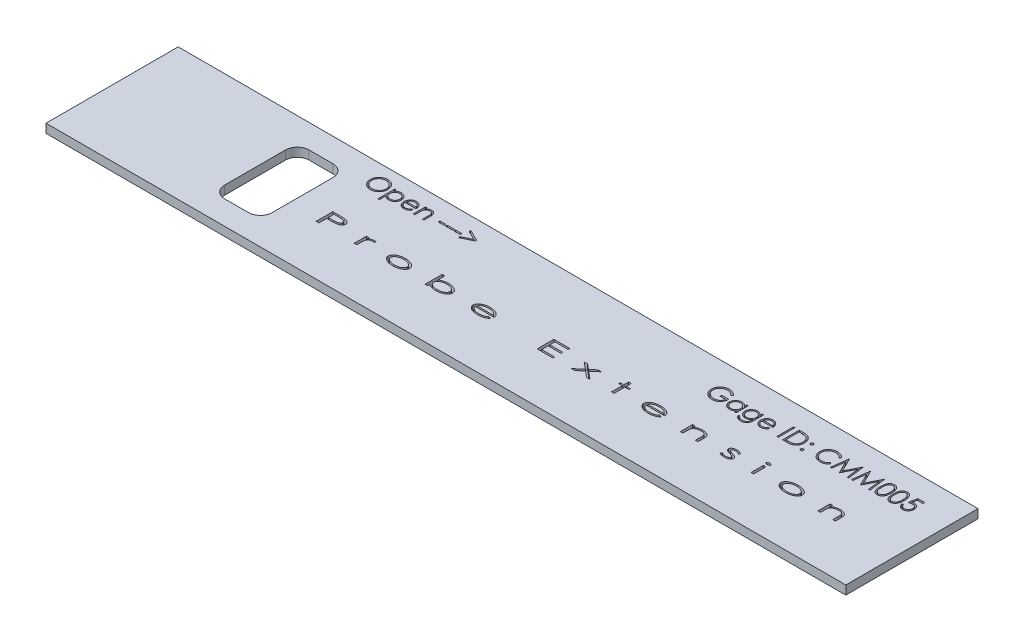
from build123d import *

# Parameters (mm, degrees)
SKETCH1_W           = 167.9
SKETCH1_H           = 27.75
BOSS_EXTRUDE1_DEPTH = 1.85
SKETCH2_W           = 10
SKETCH2_H           = 17.75
CUT_EXTRUDE1_DEPTH  = 171.187822714
FILLET1_R           = 2.5
SKETCH5_W           = 1.346153846
SKETCH5_H           = 0.358974359
SKETCH5_W_2         = 1.346153847
CUT_EXTRUDE3_DEPTH  = 1.25
SKETCH6_W           = 0.314102564
SKETCH6_H           = 3.5
CUT_EXTRUDE4_DEPTH  = 1.25
SKETCH7_W           = 0.538461539
SKETCH7_H           = 2.557692308
CUT_EXTRUDE5_DEPTH  = 1.25


with BuildPart() as part:
    # Sketch1 → Boss-Extrude1 (new body)
    with BuildSketch(Plane(origin=(0, 0, 0), x_dir=(1, 0, 0), z_dir=(0, 1, 0))):
        with Locations((83.95, 13.875)):
            Rectangle(SKETCH1_W, SKETCH1_H)
    extrude(amount=BOSS_EXTRUDE1_DEPTH)

    # Sketch2 → Cut-Extrude1 (cut, through all)
    with BuildSketch(Plane(origin=(0, 1.85, 0), x_dir=(1, 0, 0), z_dir=(0, 1, 0))):
        with Locations((35, 13.875)):
            Rectangle(SKETCH2_W, SKETCH2_H)
    extrude(amount=-CUT_EXTRUDE1_DEPTH, mode=Mode.SUBTRACT)

    # Fillet1
    fillet1_edges = [part.edges().sort_by_distance(p)[0] for p in [
        (30, 0.925, -5),
        (30, 0.925, -22.75),
        (40, 0.925, -22.75),
        (40, 0.925, -5),
    ]]
    fillet(fillet1_edges, radius=FILLET1_R)

    # Sketch5 → Cut-Extrude3 (cut)
    # profile 1 of 8: a face of its own
    with BuildSketch(Plane(origin=(0, 1.85, 0), x_dir=(1, 0, 0), z_dir=(0, 1, 0))):
        with BuildLine():
            add(Edge.make_bspline(
                [(46.08954979, 25.641462722), (46.154357896, 25.639821243), (46.281646363, 25.636597242), (46.468721261, 25.611918138), (46.647316356, 25.569222748), (46.818886495, 25.512359766), (46.981379472, 25.43650538), (47.136018364, 25.344820232), (47.282435238, 25.236343773), (47.41865662, 25.111914546), (47.54331357, 24.976531093), (47.653139456, 24.832053183), (47.74518175, 24.67935438), (47.820767537, 24.51889355), (47.880066147, 24.351033582), (47.92098519, 24.174879579), (47.94712334, 23.991572889), (47.950179118, 23.866546024), (47.951729278, 23.803121376)],
                knots=[0, 0, 0, 0, 1.065120563, 2.091984664, 3.0946048, 4.079830382, 5.057816894, 6.036188127, 7.030412546, 8.04752943, 9.064399622, 10.05169764, 11.02544977, 11.989514704, 12.962713494, 13.945757189, 14.957906945, 16, 16, 16, 16], degree=3))
            add(Edge.make_bspline(
                [(47.951729278, 23.803121376), (47.950179345, 23.74016393), (47.947124249, 23.616067509), (47.920955471, 23.433924065), (47.879914471, 23.258833368), (47.821318205, 23.091087716), (47.746092726, 22.930510152), (47.653437555, 22.777523198), (47.544296344, 22.6320767), (47.420089493, 22.495764034), (47.284688451, 22.370766564), (47.139458185, 22.261847688), (46.987664865, 22.168123563), (46.827355157, 22.09333989), (46.66065512, 22.033567969), (46.486072797, 21.992815339), (46.304426243, 21.966528296), (46.180555239, 21.96350978), (46.117594662, 21.961975543)],
                knots=[0, 0, 0, 0, 1.043624062, 2.057103931, 3.04512605, 4.022047818, 4.998200453, 5.980619268, 6.982898556, 8.009068085, 9.034988726, 10.034168286, 11.015286542, 11.987931943, 12.962482838, 13.94673481, 14.956375938, 16, 16, 16, 16], degree=3))
            add(Edge.make_bspline(
                [(46.117594662, 21.961975543), (46.054170343, 21.963524929), (45.929144127, 21.966579183), (45.745607092, 21.992760588), (45.569329348, 22.033701892), (45.400814997, 22.092211328), (45.239970067, 22.167828559), (45.086479985, 22.260032938), (44.940960837, 22.369440079), (44.804619091, 22.493606654), (44.679869893, 22.628778206), (44.571110517, 22.773612461), (44.478885404, 22.925267917), (44.403522071, 23.084165442), (44.343857612, 23.249536884), (44.303152794, 23.422485362), (44.276816842, 23.602024868), (44.273781995, 23.724267766), (44.272242098, 23.786294453)],
                knots=[0, 0, 0, 0, 1.053102029, 2.075944431, 3.073151272, 4.055350789, 5.033113405, 6.020478099, 7.024410459, 8.052272461, 9.079885166, 10.07527673, 11.055994387, 12.023226415, 12.992069828, 13.970394897, 14.97016774, 16, 16, 16, 16], degree=3))
            add(Edge.make_bspline(
                [(44.272242098, 23.786294453), (44.272776734, 23.827927122), (44.27383926, 23.910667246), (44.286630952, 24.033533846), (44.305192654, 24.154424503), (44.331794566, 24.272995451), (44.366586233, 24.388956436), (44.407638261, 24.503107199), (44.457778106, 24.614290923), (44.514458754, 24.723034314), (44.577720562, 24.82764222), (44.647596311, 24.926521803), (44.72163168, 25.0205028), (44.802795074, 25.107149804), (44.888411519, 25.18898346), (44.979869897, 25.264746177), (45.076612141, 25.335121128), (45.179054521, 25.398541469), (45.284672796, 25.455900604), (45.393549574, 25.505122455), (45.504206145, 25.547368517), (45.617160793, 25.581609342), (45.732113565, 25.608641378), (45.84931535, 25.627048731), (45.968672776, 25.639873049), (46.049084095, 25.640930551), (46.08954979, 25.641462722)],
                knots=[0, 0, 0, 0, 1.037015668, 2.060948919, 3.074880161, 4.083647147, 5.086022904, 6.090072063, 7.104153813, 8.122640571, 9.144368836, 10.147691507, 11.138137339, 12.123020368, 13.103399296, 14.087645067, 15.080126199, 16.082011238, 17.087798457, 18.072939717, 19.057185487, 20.037253025, 21.01195951, 21.997135196, 22.992090687, 24, 24, 24, 24], degree=3))
        make_face()
        with BuildLine():
            add(Edge.make_bspline(
                [(46.10497447, 25.282488363), (46.071759836, 25.282083473), (46.005648103, 25.281277563), (45.907363567, 25.270661848), (45.810371633, 25.255531959), (45.714652271, 25.233950438), (45.620605982, 25.204546385), (45.527356141, 25.170705477), (45.435753087, 25.129484386), (45.346099229, 25.082911682), (45.259184154, 25.031362761), (45.177171452, 24.974390994), (45.099848808, 24.91333244), (45.027405542, 24.848044602), (44.96005437, 24.778195001), (44.896469668, 24.704842565), (44.839200086, 24.625890673), (44.78671451, 24.543480267), (44.739746669, 24.457718685), (44.697981315, 24.369508823), (44.663817306, 24.278131136), (44.635954929, 24.184576979), (44.612855119, 24.088994519), (44.598221195, 23.99065867), (44.587488835, 23.890063558), (44.58672899, 23.822081704), (44.586344662, 23.787696696)],
                knots=[0, 0, 0, 0, 1.008559885, 2.007477868, 2.99961109, 3.989939068, 4.984837346, 5.991145699, 7.001802488, 8.033829008, 9.059044045, 10.069351652, 11.065060232, 12.050310815, 13.029377138, 14.011219647, 14.996725999, 15.989392538, 16.977580475, 17.965360261, 18.951710183, 19.937753436, 20.929683414, 21.935841486, 22.955955122, 24, 24, 24, 24], degree=3))
            add(Edge.make_bspline(
                [(44.586344662, 23.787696696), (44.587619524, 23.737134476), (44.590127572, 23.637662945), (44.612085142, 23.491894802), (44.645907117, 23.351806515), (44.695764483, 23.218164606), (44.758115098, 23.089820323), (44.835141988, 22.967912218), (44.926401074, 22.852407344), (45.0300646, 22.744112075), (45.143387307, 22.645266271), (45.263720037, 22.558502862), (45.389773644, 22.485092612), (45.521876847, 22.42528754), (45.659324386, 22.377897802), (45.803001937, 22.345419171), (45.951952397, 22.324043716), (46.053483052, 22.32199096), (46.10497447, 22.320949902)],
                knots=[0, 0, 0, 0, 1.032063989, 2.030389145, 3.003944642, 3.970395727, 4.937377036, 5.913328081, 6.909231446, 7.93887556, 8.970685674, 9.976071282, 10.964166581, 11.944589148, 12.933237628, 13.927779006, 14.949070134, 16, 16, 16, 16], degree=3))
            add(Edge.make_bspline(
                [(46.10497447, 22.320949902), (46.139583972, 22.321425406), (46.208225008, 22.322368474), (46.31032053, 22.331867151), (46.410576742, 22.34709902), (46.508853022, 22.369029676), (46.605037833, 22.396476882), (46.699532636, 22.42908461), (46.791330927, 22.469765814), (46.881590764, 22.514713765), (46.967987006, 22.565953923), (47.050462538, 22.620992073), (47.126938518, 22.681960693), (47.19932759, 22.746278506), (47.266955279, 22.815242354), (47.329364263, 22.888762576), (47.386344395, 22.967303233), (47.438810042, 23.049588639), (47.485613304, 23.135584891), (47.526392404, 23.224114569), (47.560988519, 23.314959679), (47.588917024, 23.40825125), (47.610802486, 23.503812099), (47.625882406, 23.601770177), (47.636430844, 23.701929519), (47.637225922, 23.769673375), (47.637626713, 23.803822498)],
                knots=[0, 0, 0, 0, 1.047197238, 2.076906641, 3.100256066, 4.114471768, 5.12198147, 6.126382909, 7.136867548, 8.15857795, 9.17633901, 10.174870724, 11.156907918, 12.133735059, 13.104061851, 14.077631395, 15.04955518, 16.038496417, 17.029181396, 18.010275684, 18.986308667, 19.968651475, 20.955262928, 21.950658345, 22.966943676, 24, 24, 24, 24], degree=3))
            add(Edge.make_bspline(
                [(47.637626713, 23.803822498), (47.637225601, 23.837738002), (47.636429919, 23.905015652), (47.625887444, 24.004476471), (47.610786554, 24.101729682), (47.589023846, 24.196393485), (47.560973692, 24.28849201), (47.526386362, 24.377938758), (47.485601062, 24.465066953), (47.438792838, 24.54966125), (47.386177015, 24.630835988), (47.328682771, 24.7084384), (47.265317423, 24.781011142), (47.197891398, 24.850345836), (47.124720513, 24.914963725), (47.046136219, 24.974886246), (46.963092541, 25.03155952), (46.875165306, 25.082685082), (46.784421352, 25.129899315), (46.691307394, 25.170350318), (46.596878294, 25.204722437), (46.501374182, 25.234039402), (46.403991204, 25.255447433), (46.305387375, 25.270675482), (46.205699116, 25.281273868), (46.138655896, 25.282082247), (46.10497447, 25.282488363)],
                knots=[0, 0, 0, 0, 1.02996197, 2.043119294, 3.035359645, 4.018872909, 4.991431989, 5.957985074, 6.929999688, 7.912076566, 8.892894881, 9.867085534, 10.843653904, 11.817741046, 12.803660682, 13.806313499, 14.818574707, 15.856120519, 16.894564902, 17.924820532, 18.937903209, 19.946497019, 20.957711757, 21.963978472, 22.977135795, 24, 24, 24, 24], degree=3))
        make_face(mode=Mode.SUBTRACT)
    # profile 2 of 8: a face of its own
    with BuildSketch(Plane(origin=(0, 1.85, 0), x_dir=(1, 0, 0), z_dir=(0, 1, 0))):
        with BuildLine():
            Line((48.579934406, 24.60941144), (48.89403697, 24.60941144))
            Line((48.89403697, 24.60941144), (48.89403697, 24.136154229))
            add(Edge.make_bspline(
                [(48.89403697, 24.136154229), (48.927394454, 24.179091962), (48.992218049, 24.262532855), (49.103942954, 24.370522984), (49.221869762, 24.461598287), (49.349033175, 24.53298082), (49.483456865, 24.586801632), (49.624589182, 24.626581082), (49.773627947, 24.650022557), (49.8755244, 24.652844218), (49.927490496, 24.654283235)],
                knots=[0, 0, 0, 0, 1.0828784, 2.104357462, 3.088488658, 4.04616522, 5.001424249, 5.969181776, 6.964304535, 8, 8, 8, 8], degree=3))
            add(Edge.make_bspline(
                [(49.927490496, 24.654283235), (49.972882099, 24.652970056), (50.062600987, 24.650374489), (50.194664216, 24.632801434), (50.321839599, 24.602683742), (50.443407653, 24.559282827), (50.560670719, 24.505627357), (50.671892818, 24.437910321), (50.778806374, 24.35950413), (50.878722563, 24.269271979), (50.971043931, 24.171643713), (51.050890112, 24.066621409), (51.119762016, 23.957658823), (51.175432313, 23.84306673), (51.21904066, 23.7237475), (51.250055338, 23.59921906), (51.268512981, 23.469943119), (51.270989433, 23.382040399), (51.272242098, 23.337576504)],
                knots=[0, 0, 0, 0, 1.041296284, 2.058176809, 3.050446431, 4.034000596, 5.01514041, 6.003636468, 7.015969324, 8.052561599, 9.08815499, 10.094063707, 11.074456064, 12.040834395, 13.011057502, 13.983766392, 14.980127149, 16, 16, 16, 16], degree=3))
            add(Edge.make_bspline(
                [(51.272242098, 23.337576504), (51.271016613, 23.292174196), (51.268599778, 23.202634291), (51.249854772, 23.071147194), (51.219897898, 22.94465982), (51.176839715, 22.823382556), (51.121198227, 22.707398905), (51.053493666, 22.596792509), (50.973607199, 22.491598806), (50.882306071, 22.393245906), (50.783253135, 22.302646593), (50.677375646, 22.223408523), (50.56631672, 22.156867148), (50.450644553, 22.101284189), (50.329368915, 22.059392004), (50.203055637, 22.029174204), (50.071773491, 22.010539708), (49.982472339, 22.008087566), (49.937306201, 22.006847337)],
                knots=[0, 0, 0, 0, 1.038740735, 2.04854663, 3.033179607, 4.009277356, 4.987731542, 5.972001279, 6.972200261, 8.005528982, 9.039189865, 10.040446548, 11.026516639, 11.997840187, 12.972163198, 13.956796175, 14.96660207, 16, 16, 16, 16], degree=3))
            add(Edge.make_bspline(
                [(49.937306201, 22.006847337), (49.886478629, 22.008142145), (49.786079273, 22.01069977), (49.639281602, 22.03661918), (49.49800475, 22.075356116), (49.363813926, 22.132055109), (49.235646113, 22.204310625), (49.114226307, 22.292420831), (48.998909554, 22.396201456), (48.929500797, 22.474933272), (48.89403697, 22.515160639)],
                knots=[0, 0, 0, 0, 1.014726462, 2.004382257, 2.969841629, 3.936926163, 4.907207904, 5.903978561, 6.929055279, 8, 8, 8, 8], degree=3))
            Line((48.89403697, 22.515160639), (48.89403697, 21.10941144))
            Line((48.89403697, 21.10941144), (48.579934406, 21.10941144))
            Line((48.579934406, 21.10941144), (48.579934406, 24.60941144))
        make_face()
        with BuildLine():
            add(Edge.make_bspline(
                [(49.924686008, 24.340180671), (49.889106446, 24.339540413), (49.819059458, 24.338279909), (49.716387239, 24.32330596), (49.617491811, 24.301568219), (49.52336986, 24.268656319), (49.433119243, 24.228257506), (49.347435079, 24.177775495), (49.266377511, 24.118123489), (49.190150481, 24.050444145), (49.121287187, 23.975869457), (49.060324259, 23.896281648), (49.009116954, 23.811781508), (48.966614934, 23.723156145), (48.934271651, 23.62971086), (48.911315932, 23.531977848), (48.896885579, 23.429850135), (48.894996641, 23.360294129), (48.89403697, 23.324956312)],
                knots=[0, 0, 0, 0, 1.05670511, 2.080379991, 3.077984906, 4.06214886, 5.038337365, 6.01289324, 7.01187578, 8.025460281, 9.038092164, 10.024533457, 11.000252242, 11.969694649, 12.940728589, 13.933144304, 14.949937299, 16, 16, 16, 16], degree=3))
            add(Edge.make_bspline(
                [(48.89403697, 23.324956312), (48.895627826, 23.278568199), (48.898744448, 23.187689958), (48.924081816, 23.054905836), (48.96531708, 22.929254181), (49.023845794, 22.811793144), (49.097793368, 22.703810309), (49.186891524, 22.607119702), (49.290334075, 22.522329111), (49.406401267, 22.450907857), (49.530823398, 22.392919791), (49.66060931, 22.351405581), (49.793974191, 22.325833352), (49.88414251, 22.322586533), (49.929593861, 22.320949902)],
                knots=[0, 0, 0, 0, 1.03728447, 2.032128127, 3.01272805, 3.987917167, 4.958271349, 5.931593992, 6.91984656, 7.941419022, 8.973179163, 9.983609215, 10.983593296, 12, 12, 12, 12], degree=3))
            add(Edge.make_bspline(
                [(49.929593861, 22.320949902), (49.974129629, 22.322506278), (50.062525122, 22.325595407), (50.192683243, 22.352333594), (50.319173882, 22.393178619), (50.439354054, 22.452738175), (50.552177542, 22.525728233), (50.654059096, 22.613288267), (50.743066009, 22.71477821), (50.818930364, 22.827786713), (50.880061849, 22.948962096), (50.925992089, 23.074343485), (50.952500663, 23.203488908), (50.956257451, 23.290486621), (50.958139534, 23.334070895)],
                knots=[0, 0, 0, 0, 1.00104056, 1.986885549, 2.97790532, 3.984399681, 4.995088187, 5.994304198, 6.996462723, 8.023150851, 9.048424203, 10.043036403, 11.019596776, 12, 12, 12, 12], degree=3))
            add(Edge.make_bspline(
                [(50.958139534, 23.334070895), (50.9566848, 23.377925884), (50.953786666, 23.465294188), (50.925239629, 23.594057091), (50.882339651, 23.719945067), (50.819780599, 23.839465617), (50.74557933, 23.952239699), (50.655832333, 24.051793578), (50.555216136, 24.138964251), (50.442526972, 24.210979661), (50.321586547, 24.268265156), (50.194271631, 24.310148795), (50.061228028, 24.335322544), (49.970600374, 24.338547051), (49.924686008, 24.340180671)],
                knots=[0, 0, 0, 0, 0.983928682, 1.960191568, 2.949917689, 3.96440592, 4.982380491, 5.975291189, 6.965713506, 7.964880129, 8.970154049, 9.96478489, 10.968906225, 12, 12, 12, 12], degree=3))
        make_face(mode=Mode.SUBTRACT)
    # profile 3 of 8: a face of its own
    with BuildSketch(Plane(origin=(0, 1.85, 0), x_dir=(1, 0, 0), z_dir=(0, 1, 0))):
        with BuildLine():
            Line((53.99960588, 22.85941144), (54.278652355, 22.712876985))
            add(Edge.make_bspline(
                [(54.278652355, 22.712876985), (54.256415759, 22.673433654), (54.213152151, 22.596692551), (54.138751403, 22.49126069), (54.06075933, 22.396412975), (53.975655362, 22.31468332), (53.885985683, 22.243431935), (53.791253029, 22.181094111), (53.690964211, 22.12797559), (53.585114486, 22.083223062), (53.472814935, 22.048813568), (53.353793419, 22.024509347), (53.227821923, 22.009486079), (53.141475743, 22.007740938), (53.09726213, 22.006847337)],
                knots=[0, 0, 0, 0, 1.120438281, 2.179929193, 3.190490725, 4.156257408, 5.095198341, 6.022838206, 6.959905092, 7.901321166, 8.864066838, 9.862729781, 10.905609505, 12, 12, 12, 12], degree=3))
            add(Edge.make_bspline(
                [(53.09726213, 22.006847337), (53.048120153, 22.007994513), (52.952258391, 22.01023232), (52.812718644, 22.029524784), (52.681339225, 22.060997143), (52.558127522, 22.104962684), (52.44338527, 22.162390008), (52.336884415, 22.23234949), (52.238064889, 22.314481745), (52.15004068, 22.409498188), (52.070796797, 22.511180146), (52.000870977, 22.61713603), (51.942413546, 22.727099254), (51.894860936, 22.840369779), (51.856456071, 22.956233672), (51.829689367, 23.07574514), (51.814259619, 23.198580724), (51.811895173, 23.28167806), (51.810703637, 23.323554068)],
                knots=[0, 0, 0, 0, 1.145258523, 2.234067595, 3.276747158, 4.290159414, 5.277019952, 6.260822364, 7.254936242, 8.264827045, 9.274100331, 10.257902744, 11.220704747, 12.172965371, 13.118907548, 14.062713208, 15.023725156, 16, 16, 16, 16], degree=3))
            add(Edge.make_bspline(
                [(51.810703637, 23.323554068), (51.811762778, 23.362848899), (51.813861856, 23.440726063), (51.827092644, 23.555991608), (51.850540937, 23.66802006), (51.882717261, 23.776904508), (51.924268507, 23.882462642), (51.975100726, 23.984758706), (52.035293104, 24.083683846), (52.081765778, 24.14608698), (52.10517479, 24.177520414)],
                knots=[0, 0, 0, 0, 1.024358464, 2.0301432, 3.019427413, 4.004406732, 4.986367066, 5.972626655, 6.978780325, 8, 8, 8, 8], degree=3))
            add(Edge.make_bspline(
                [(52.10517479, 24.177520414), (52.136882473, 24.215389284), (52.19929342, 24.289927435), (52.304849775, 24.387865761), (52.419149971, 24.469909536), (52.540761598, 24.537916672), (52.671098072, 24.589590319), (52.808407363, 24.628097901), (52.954252949, 24.649675912), (53.05395817, 24.652723746), (53.10497447, 24.654283235)],
                knots=[0, 0, 0, 0, 1.030682036, 2.02871468, 2.997146059, 3.962720338, 4.930598197, 5.918074684, 6.934738563, 8, 8, 8, 8], degree=3))
            add(Edge.make_bspline(
                [(53.10497447, 24.654283235), (53.157422075, 24.652929186), (53.260312321, 24.650272851), (53.410344442, 24.625646517), (53.552305159, 24.586593963), (53.686137663, 24.531440172), (53.811855524, 24.46028062), (53.928641573, 24.372138779), (54.038493086, 24.269720692), (54.102401665, 24.190957482), (54.134922387, 24.150877786)],
                knots=[0, 0, 0, 0, 1.056321875, 2.072262726, 3.055038591, 4.01806755, 4.982017516, 5.957941055, 6.960871419, 8, 8, 8, 8], degree=3))
            add(Edge.make_bspline(
                [(54.134922387, 24.150877786), (54.157049325, 24.120674205), (54.201155918, 24.060468086), (54.256403018, 23.962296929), (54.304360413, 23.859586335), (54.342693374, 23.750676038), (54.373732875, 23.636856457), (54.396189694, 23.517313913), (54.409359313, 23.392084001), (54.41194801, 23.306757446), (54.413267739, 23.263257594)],
                knots=[0, 0, 0, 0, 0.94817472, 1.890038105, 2.849395472, 3.817997239, 4.812318967, 5.836947057, 6.897266129, 8, 8, 8, 8], degree=3))
            Line((54.413267739, 23.263257594), (52.124806201, 23.263257594))
            add(Edge.make_bspline(
                [(52.124806201, 23.263257594), (52.126345807, 23.22955713), (52.129373381, 23.163286526), (52.143488524, 23.066315743), (52.165737298, 22.973942401), (52.197006361, 22.886859359), (52.234873206, 22.803929231), (52.281258923, 22.725767194), (52.336598477, 22.652729264), (52.398324176, 22.584162127), (52.467031271, 22.523101365), (52.539314019, 22.468449589), (52.616207584, 22.422643992), (52.697105667, 22.385464103), (52.781877452, 22.356357787), (52.870549647, 22.336489966), (52.962947764, 22.323182859), (53.025933498, 22.321703194), (53.05799931, 22.320949902)],
                knots=[0, 0, 0, 0, 1.094153842, 2.151609401, 3.174256925, 4.172055639, 5.149267565, 6.128595816, 7.11444997, 8.118368179, 9.117203808, 10.09244225, 11.054858984, 12.015122123, 12.976791628, 13.957293641, 14.960065497, 16, 16, 16, 16], degree=3))
            add(Edge.make_bspline(
                [(53.05799931, 22.320949902), (53.089350457, 22.321557958), (53.151557148, 22.322764459), (53.244198006, 22.33449637), (53.335337533, 22.353466646), (53.424598516, 22.379356636), (53.510169362, 22.410933488), (53.589414912, 22.449036346), (53.662295128, 22.491186092), (53.730412094, 22.539395767), (53.796483088, 22.598403954), (53.862025574, 22.672039675), (53.932302228, 22.759127203), (53.97629182, 22.824672869), (53.99960588, 22.85941144)],
                knots=[0, 0, 0, 0, 0.99110716, 1.966546729, 2.947904876, 3.932708344, 4.903319531, 5.828989031, 6.710028674, 7.56322171, 8.463672341, 9.504779593, 10.677557249, 12, 12, 12, 12], degree=3))
        make_face()
        with BuildLine():
            add(Edge.make_bspline(
                [(54.099165175, 23.577360158), (54.08766855, 23.619023032), (54.065541249, 23.699210652), (54.019304885, 23.810251543), (53.967233344, 23.908939444), (53.905611612, 23.994519077), (53.835792887, 24.07052259), (53.755147704, 24.136941175), (53.664711811, 24.196358626), (53.56495267, 24.246511125), (53.459310885, 24.289200984), (53.348704693, 24.3178261), (53.235846905, 24.337435642), (53.159512619, 24.339261751), (53.121100271, 24.340180671)],
                knots=[0, 0, 0, 0, 1.154881502, 2.222775134, 3.210006277, 4.132804581, 5.035138423, 5.962687519, 6.919655026, 7.923214229, 8.944639381, 9.960483929, 10.97369054, 12, 12, 12, 12], degree=3))
            add(Edge.make_bspline(
                [(53.121100271, 24.340180671), (53.089750833, 24.339568999), (53.027779584, 24.338359853), (52.936478515, 24.326889724), (52.848798817, 24.307929879), (52.764093529, 24.281964922), (52.683472661, 24.24735632), (52.605277892, 24.206773093), (52.531497496, 24.157231509), (52.485356201, 24.119472655), (52.462045784, 24.100397017)],
                knots=[0, 0, 0, 0, 1.04873581, 2.073130211, 3.073294108, 4.04793562, 5.032784715, 6.005352987, 6.992311501, 8, 8, 8, 8], degree=3))
            add(Edge.make_bspline(
                [(52.462045784, 24.100397017), (52.445352502, 24.085302701), (52.411569368, 24.054755485), (52.366428846, 24.002126279), (52.323208374, 23.945374717), (52.283874721, 23.882329592), (52.247797134, 23.813708813), (52.214037157, 23.740091178), (52.183650745, 23.660918047), (52.166554635, 23.605745608), (52.157758925, 23.577360158)],
                knots=[0, 0, 0, 0, 0.879870761, 1.780643979, 2.707998968, 3.669668524, 4.684282772, 5.740141944, 6.837334558, 8, 8, 8, 8], degree=3))
            Line((52.157758925, 23.577360158), (54.099165175, 23.577360158))
        make_face(mode=Mode.SUBTRACT)
    # profile 4 of 8: a face of its own
    with BuildSketch(Plane(origin=(0, 1.85, 0), x_dir=(1, 0, 0), z_dir=(0, 1, 0))):
        with BuildLine():
            Line((55.041472867, 24.60941144), (55.355575431, 24.60941144))
            Line((55.355575431, 24.60941144), (55.355575431, 24.148073299))
            add(Edge.make_bspline(
                [(55.355575431, 24.148073299), (55.389113067, 24.189916022), (55.454194018, 24.271113285), (55.562578351, 24.37783386), (55.677122251, 24.465779085), (55.797124255, 24.535882879), (55.922747265, 24.588729505), (56.053225535, 24.626895436), (56.189340241, 24.649780265), (56.281904678, 24.652770495), (56.328732483, 24.654283235)],
                knots=[0, 0, 0, 0, 1.12780773, 2.188550248, 3.19190651, 4.159438251, 5.104880172, 6.052711206, 7.014878035, 8, 8, 8, 8], degree=3))
            add(Edge.make_bspline(
                [(56.328732483, 24.654283235), (56.376063117, 24.652538039), (56.468700585, 24.649122271), (56.603578646, 24.62210558), (56.72955204, 24.575960325), (56.846171595, 24.512748254), (56.951298809, 24.434141781), (57.04362366, 24.342563999), (57.119986908, 24.237227916), (57.171184271, 24.13950476), (57.204909918, 24.052815965), (57.226142256, 23.978569215), (57.244173237, 23.895851064), (57.259804985, 23.804911475), (57.270382097, 23.705113285), (57.278724389, 23.596865593), (57.284703083, 23.480203462), (57.28494029, 23.399516835), (57.285062611, 23.357909036)],
                knots=[0, 0, 0, 0, 1.235846778, 2.418850247, 3.575807741, 4.728682307, 5.871620074, 6.994088408, 8.11269785, 9.256955736, 9.865816715, 10.540099792, 11.271859618, 12.076849838, 12.949306005, 13.892391288, 14.913166135, 16, 16, 16, 16], degree=3))
            Line((57.285062611, 23.357909036), (57.285062611, 22.051719132))
            Line((57.285062611, 22.051719132), (56.970960047, 22.051719132))
            Line((56.970960047, 22.051719132), (56.970960047, 23.254844132))
            add(Edge.make_bspline(
                [(56.970960047, 23.254844132), (56.970766839, 23.289666577), (56.970397265, 23.356275988), (56.969231618, 23.451645011), (56.966421811, 23.53813159), (56.962473499, 23.615528957), (56.956694468, 23.683762794), (56.950671837, 23.74297207), (56.94330686, 23.793081613), (56.936743947, 23.823246695), (56.933800592, 23.836775222)],
                knots=[0, 0, 0, 0, 1.430800155, 2.736877192, 3.918605307, 4.986035426, 5.920637409, 6.731861385, 7.431261377, 8, 8, 8, 8], degree=3))
            add(Edge.make_bspline(
                [(56.933800592, 23.836775222), (56.92317506, 23.876486407), (56.9027242, 23.952918152), (56.852190216, 24.056592504), (56.788376036, 24.144790692), (56.710478186, 24.216967414), (56.619249111, 24.27313825), (56.514941968, 24.312112205), (56.398563327, 24.336488474), (56.316708944, 24.338915606), (56.274044983, 24.340180671)],
                knots=[0, 0, 0, 0, 1.084156227, 2.086665306, 3.027808233, 3.945421172, 4.874247719, 5.839848303, 6.874090471, 8, 8, 8, 8], degree=3))
            add(Edge.make_bspline(
                [(56.274044983, 24.340180671), (56.248777299, 24.339704666), (56.198773206, 24.338762665), (56.124623234, 24.329311367), (56.052699061, 24.313852912), (55.982278852, 24.292984274), (55.914771058, 24.264322005), (55.848006767, 24.231792635), (55.784500003, 24.191244423), (55.722896606, 24.146053801), (55.665583798, 24.095974594), (55.61225546, 24.043130084), (55.56471744, 23.98685448), (55.521648764, 23.928054533), (55.484470501, 23.865922695), (55.452017413, 23.801058388), (55.424481718, 23.733376239), (55.410799026, 23.686401178), (55.403952835, 23.662897017)],
                knots=[0, 0, 0, 0, 1.023777757, 2.026029729, 3.023749952, 4.003683103, 4.997618607, 5.993177895, 7.010360494, 8.046726602, 9.087585522, 10.09234134, 11.086953743, 12.070360549, 13.043493632, 14.017870808, 15.008233677, 16, 16, 16, 16], degree=3))
            add(Edge.make_bspline(
                [(55.403952835, 23.662897017), (55.400013187, 23.645641814), (55.391436778, 23.60807814), (55.382173598, 23.54643372), (55.373766023, 23.475123745), (55.366729064, 23.394231428), (55.362423648, 23.303473553), (55.357729251, 23.203237715), (55.35602019, 23.093124227), (55.355727836, 23.016462534), (55.355575431, 22.97649878)],
                knots=[0, 0, 0, 0, 0.615963638, 1.340920617, 2.168419149, 3.115676021, 4.16674242, 5.331190069, 6.6087489, 8, 8, 8, 8], degree=3))
            Line((55.355575431, 22.97649878), (55.355575431, 22.051719132))
            Line((55.355575431, 22.051719132), (55.041472867, 22.051719132))
            Line((55.041472867, 22.051719132), (55.041472867, 24.60941144))
        make_face()
    # profile 5 of 8: a face of its own
    with BuildSketch(Plane(origin=(0, 1.85, 0), x_dir=(1, 0, 0), z_dir=(0, 1, 0))):
        with Locations((59.797883124, 23.397872979)):
            Rectangle(SKETCH5_W, SKETCH5_H)
    # profile 6 of 8: a face of its own
    with BuildSketch(Plane(origin=(0, 1.85, 0), x_dir=(1, 0, 0), z_dir=(0, 1, 0))):
        with Locations((61.413267739, 23.397872979)):
            Rectangle(SKETCH5_W, SKETCH5_H)
    # profile 7 of 8: a face of its own
    with BuildSketch(Plane(origin=(0, 1.85, 0), x_dir=(1, 0, 0), z_dir=(0, 1, 0))):
        with Locations((63.028652355, 23.397872979)):
            Rectangle(SKETCH5_W_2, SKETCH5_H)
    # profile 8 of 8: a face of its own
    with BuildSketch(Plane(origin=(0, 1.85, 0), x_dir=(1, 0, 0), z_dir=(0, 1, 0))):
        Polygon((64.105575431, 22.841883395), (66.070118701, 23.779283235), (64.105575431, 24.716683075), (64.105575431, 25.058129389), (66.528652355, 23.901979549), (66.528652355, 23.656586921), (64.105575431, 22.500437081), align=None)
    extrude(amount=-CUT_EXTRUDE3_DEPTH, mode=Mode.SUBTRACT)

    # Sketch6 → Cut-Extrude4 (cut)
    # profile 1 of 14: a face of its own
    with BuildSketch(Plane(origin=(0, 1.85, 0), x_dir=(1, 0, 0), z_dir=(0, 1, 0))):
        with BuildLine():
            Line((121.636021821, 22.660884244), (121.366791052, 22.40567591))
            add(Edge.make_bspline(
                [(121.366791052, 22.40567591), (121.318072164, 22.451506773), (121.221796117, 22.542075636), (121.064835875, 22.659586631), (120.901072241, 22.760252732), (120.731359744, 22.842158968), (120.55990119, 22.907511729), (120.388972414, 22.954039869), (120.220326712, 22.983712406), (120.108159494, 22.987260776), (120.052888808, 22.989009244)],
                knots=[0, 0, 0, 0, 1.08915593, 2.152340314, 3.188132944, 4.216796309, 5.218260357, 6.173443236, 7.099959455, 8, 8, 8, 8], degree=3))
            add(Edge.make_bspline(
                [(120.052888808, 22.989009244), (120.018974109, 22.988595638), (119.951232668, 22.987769499), (119.850610724, 22.977225284), (119.751044087, 22.962060419), (119.652720712, 22.940118542), (119.555449426, 22.912309482), (119.459568534, 22.877524019), (119.364899179, 22.836968775), (119.272333098, 22.790106301), (119.182592594, 22.738626455), (119.097835759, 22.681577914), (119.01752236, 22.620789124), (118.943161934, 22.554738145), (118.874326748, 22.484023279), (118.809378376, 22.409959973), (118.75060108, 22.330524755), (118.697509915, 22.247179129), (118.650148296, 22.161386939), (118.608339643, 22.07397395), (118.573242555, 21.985230095), (118.5454731, 21.895044018), (118.522562446, 21.804113428), (118.506444838, 21.711808707), (118.497358116, 21.618031022), (118.495786336, 21.555233763), (118.49499618, 21.523664692)],
                knots=[0, 0, 0, 0, 1.02818874, 2.053710826, 3.065248034, 4.081641283, 5.106893873, 6.131558223, 7.173050175, 8.228653731, 9.27666206, 10.308777013, 11.325269123, 12.329503258, 13.32196095, 14.316845687, 15.314881793, 16.315733098, 17.311955233, 18.285320748, 19.252783886, 20.203351036, 21.145449891, 22.095197417, 23.042428769, 24, 24, 24, 24], degree=3))
            add(Edge.make_bspline(
                [(118.49499618, 21.523664692), (118.495751899, 21.491393875), (118.497261271, 21.426940362), (118.506921591, 21.330746289), (118.524849831, 21.235980887), (118.54881754, 21.142332754), (118.578798356, 21.049641506), (118.616171022, 20.958308996), (118.660436623, 20.868338605), (118.711673175, 20.780540988), (118.767859378, 20.695017964), (118.830802459, 20.614458443), (118.897663043, 20.537789665), (118.970876942, 20.466713902), (119.048096485, 20.399330005), (119.131628761, 20.337494483), (119.219831221, 20.28001626), (119.312838433, 20.227619741), (119.409641215, 20.180811205), (119.508897968, 20.139187309), (119.610925784, 20.104907972), (119.715188474, 20.076969868), (119.821561745, 20.05406957), (119.930585548, 20.03933709), (120.041458257, 20.028646259), (120.116196889, 20.027864589), (120.153850347, 20.027470782)],
                knots=[0, 0, 0, 0, 0.93586088, 1.869166235, 2.799637598, 3.729985548, 4.670839027, 5.622275134, 6.589130586, 7.576015415, 8.568469353, 9.55398029, 10.53834874, 11.515998671, 12.510579167, 13.508179873, 14.527009472, 15.561807829, 16.601455013, 17.643573243, 18.680854198, 19.719860599, 20.772568776, 21.833555941, 22.908541556, 24, 24, 24, 24], degree=3))
            add(Edge.make_bspline(
                [(120.153850347, 20.027470782), (120.199228694, 20.028419359), (120.288336451, 20.030282042), (120.419322894, 20.044782332), (120.545125965, 20.067429125), (120.665392168, 20.100595022), (120.780261189, 20.142898697), (120.89015413, 20.193894083), (120.994205789, 20.255537143), (121.092728962, 20.32511101), (121.183486148, 20.402625842), (121.265340272, 20.486270297), (121.336985761, 20.575638364), (121.39949046, 20.670203679), (121.451199115, 20.770748984), (121.49364191, 20.876781547), (121.526175201, 20.988349059), (121.539530176, 21.06544069), (121.546278232, 21.104393859)],
                knots=[0, 0, 0, 0, 1.13008108, 2.219097802, 3.278683437, 4.311054135, 5.322181354, 6.324827112, 7.324222904, 8.330512327, 9.32562643, 10.293043162, 11.24128371, 12.174520618, 13.111833804, 14.052305215, 15.015860969, 16, 16, 16, 16], degree=3))
            Line((121.546278232, 21.104393859), (120.379611565, 21.104393859))
            Line((120.379611565, 21.104393859), (120.379611565, 21.463368218))
            Line((120.379611565, 21.463368218), (121.860380796, 21.463368218))
            add(Edge.make_bspline(
                [(121.860380796, 21.463368218), (121.858674947, 21.396460729), (121.855336294, 21.265510688), (121.831917378, 21.074540417), (121.794100866, 20.894168723), (121.742440554, 20.724205652), (121.675565274, 20.564892059), (121.594192745, 20.416066193), (121.497020624, 20.278689512), (121.387510183, 20.151640508), (121.264610225, 20.038311296), (121.131641605, 19.938705358), (120.988384637, 19.854802743), (120.834974829, 19.78654208), (120.671914396, 19.733268086), (120.498826016, 19.695496509), (120.315944415, 19.672866546), (120.190607738, 19.669975166), (120.126506597, 19.668496423)],
                knots=[0, 0, 0, 0, 1.140356446, 2.231883559, 3.274166699, 4.278491846, 5.25512956, 6.21435461, 7.1637429, 8.11826594, 9.068280886, 10.0076534, 10.945064095, 11.891975133, 12.864533718, 13.863980011, 14.907571808, 16, 16, 16, 16], degree=3))
            add(Edge.make_bspline(
                [(120.126506597, 19.668496423), (120.086996462, 19.669065544), (120.009069741, 19.670188035), (119.893978813, 19.678165382), (119.782061192, 19.690445959), (119.673333183, 19.708991082), (119.567394841, 19.731705736), (119.464775256, 19.760792455), (119.365083514, 19.794461154), (119.268165528, 19.832756828), (119.174900982, 19.877128485), (119.084874465, 19.926438124), (118.997588339, 19.980431485), (118.913637174, 20.040042331), (118.832583552, 20.104824791), (118.754950109, 20.17490871), (118.680302231, 20.250079829), (118.633541767, 20.303458839), (118.609980155, 20.330355398)],
                knots=[0, 0, 0, 0, 1.107784379, 2.184907829, 3.233506516, 4.263428166, 5.276301166, 6.270063455, 7.25232949, 8.225834625, 9.190232166, 10.146266622, 11.1027726, 12.066435141, 13.031522626, 14.010570082, 14.99756817, 16, 16, 16, 16], degree=3))
            add(Edge.make_bspline(
                [(118.609980155, 20.330355398), (118.575794223, 20.373026051), (118.50798981, 20.457659068), (118.420711653, 20.593259012), (118.346310251, 20.733660872), (118.285942428, 20.879255501), (118.238804342, 21.029906714), (118.204998089, 21.185422005), (118.1851908, 21.346001635), (118.182337263, 21.4546669), (118.180893616, 21.509642257)],
                knots=[0, 0, 0, 0, 1.023165419, 2.029347347, 3.013907458, 3.994755782, 4.975994455, 5.96558838, 6.970761222, 8, 8, 8, 8], degree=3))
            add(Edge.make_bspline(
                [(118.180893616, 21.509642257), (118.181425854, 21.550808509), (118.182483566, 21.632617817), (118.195309082, 21.754075124), (118.2137105, 21.873375816), (118.240757555, 21.990422373), (118.27485382, 22.105292964), (118.317407306, 22.218040928), (118.366952202, 22.3287328), (118.424537698, 22.436606668), (118.488622157, 22.540231081), (118.558172378, 22.639188884), (118.634175978, 22.731677949), (118.715391777, 22.818869597), (118.802788768, 22.899668444), (118.895548191, 22.974822555), (118.993741534, 23.044432741), (119.097677714, 23.107402575), (119.205805398, 23.163966196), (119.3178654, 23.213555408), (119.433823511, 23.254538723), (119.552810988, 23.289312503), (119.675728489, 23.315027643), (119.801684026, 23.333676389), (119.931334138, 23.346436988), (120.018970167, 23.347463244), (120.063405635, 23.347983603)],
                knots=[0, 0, 0, 0, 1.008945113, 2.00506715, 2.99143336, 3.967273523, 4.948097931, 5.927297278, 6.919902385, 7.919676788, 8.923139349, 9.905703106, 10.883022732, 11.856032218, 12.825136022, 13.798837087, 14.781400844, 15.773989409, 16.776158564, 17.77167057, 18.775803737, 19.789618931, 20.80898985, 21.851988756, 22.910860228, 24, 24, 24, 24], degree=3))
            add(Edge.make_bspline(
                [(120.063405635, 23.347983603), (120.099643879, 23.347404111), (120.171500058, 23.346255047), (120.27842579, 23.338290399), (120.383698805, 23.325666518), (120.487475195, 23.308439731), (120.589401561, 23.284976041), (120.689768266, 23.256897756), (120.788720803, 23.224205933), (120.885949052, 23.185217087), (120.982106768, 23.140963462), (121.077728608, 23.09115004), (121.172487854, 23.034925035), (121.266548836, 22.9721215), (121.360504694, 22.903818082), (121.452869336, 22.828061258), (121.54587228, 22.747838502), (121.605674094, 22.690156318), (121.636021821, 22.660884244)],
                knots=[0, 0, 0, 0, 0.985871117, 1.954866573, 2.915460327, 3.869826059, 4.81536089, 5.759505086, 6.70452669, 7.649098992, 8.607881297, 9.583363685, 10.581137262, 11.603961102, 12.659522466, 13.73993555, 14.853081303, 16, 16, 16, 16], degree=3))
        make_face()
    # profile 2 of 14: a face of its own
    with BuildSketch(Plane(origin=(0, 1.85, 0), x_dir=(1, 0, 0), z_dir=(0, 1, 0))):
        with BuildLine():
            Line((125.091150026, 22.315932321), (125.091150026, 19.758240013))
            Line((125.091150026, 19.758240013), (124.777047462, 19.758240013))
            Line((124.777047462, 19.758240013), (124.777047462, 20.200647866))
            add(Edge.make_bspline(
                [(124.777047462, 20.200647866), (124.741628672, 20.160608272), (124.672508456, 20.0824705), (124.557067338, 19.980388328), (124.434699161, 19.896010006), (124.305997839, 19.827860091), (124.171079596, 19.776668034), (124.030243509, 19.740281875), (123.883432128, 19.71688804), (123.783179773, 19.714552018), (123.732375988, 19.713368218)],
                knots=[0, 0, 0, 0, 1.074387032, 2.096679803, 3.090159297, 4.057316773, 5.018401886, 5.985159533, 6.978961417, 8, 8, 8, 8], degree=3))
            add(Edge.make_bspline(
                [(123.732375988, 19.713368218), (123.687208034, 19.71459459), (123.598134829, 19.717013051), (123.467105752, 19.735775354), (123.341013503, 19.765905976), (123.21973893, 19.807806866), (123.104066785, 19.863387687), (122.993006688, 19.929928935), (122.887133996, 20.009169765), (122.788062457, 20.099757794), (122.696830457, 20.198152781), (122.616769184, 20.303098328), (122.550016104, 20.414140632), (122.494196023, 20.529873785), (122.451199679, 20.651188705), (122.421226045, 20.777665873), (122.402485598, 20.909155747), (122.400068137, 20.99869527), (122.398842334, 21.044097385)],
                knots=[0, 0, 0, 0, 1.033919861, 2.038935746, 3.024066025, 3.998881131, 4.97069526, 5.957263378, 6.95902576, 7.993208707, 9.027059324, 10.027763471, 11.009749337, 11.988697705, 12.965288445, 13.950418724, 14.960734635, 16, 16, 16, 16], degree=3))
            add(Edge.make_bspline(
                [(122.398842334, 21.044097385), (122.400095305, 21.088561088), (122.402572362, 21.176463432), (122.421025582, 21.30574213), (122.452056591, 21.43026039), (122.495604438, 21.549617334), (122.551446393, 21.663957384), (122.61937448, 21.773361409), (122.699393605, 21.878130806), (122.791646012, 21.975802033), (122.891580782, 22.066022647), (122.998489513, 22.144431693), (123.109712795, 22.212148542), (123.226975805, 22.265802018), (123.34854291, 22.309211122), (123.475496356, 22.339244091), (123.607307934, 22.356941412), (123.696798426, 22.359504176), (123.742191693, 22.360804116)],
                knots=[0, 0, 0, 0, 1.020392517, 2.01726096, 2.990465484, 3.961182959, 4.928053699, 5.906110375, 6.912531644, 7.948652711, 8.985773172, 9.998621852, 10.987621588, 11.969261332, 12.953316658, 13.946091881, 14.958173133, 16, 16, 16, 16], degree=3))
            add(Edge.make_bspline(
                [(123.742191693, 22.360804116), (123.794391552, 22.359366364), (123.896753012, 22.356547001), (124.046481021, 22.333084274), (124.188125499, 22.293445807), (124.322779851, 22.239528309), (124.449960537, 22.16787958), (124.568463522, 22.077499618), (124.679529005, 21.968958432), (124.743909297, 21.885587987), (124.777047462, 21.842675109)],
                knots=[0, 0, 0, 0, 1.038897134, 2.037228247, 3.008116434, 3.962042015, 4.918381754, 5.904844433, 6.921570401, 8, 8, 8, 8], degree=3))
            Line((124.777047462, 21.842675109), (124.777047462, 22.315932321))
            Line((124.777047462, 22.315932321), (125.091150026, 22.315932321))
        make_face()
        with BuildLine():
            add(Edge.make_bspline(
                [(123.746398424, 22.046701551), (123.700484086, 22.045067914), (123.609856486, 22.041843373), (123.476812484, 22.016669877), (123.34949907, 21.974785283), (123.228552996, 21.917503382), (123.115884779, 21.845474645), (123.015191108, 21.758353262), (122.925648407, 21.658516248), (122.850340143, 21.546414137), (122.788949646, 21.426236046), (122.745782614, 21.300611608), (122.717313366, 21.171806631), (122.714404846, 21.084443945), (122.712944898, 21.040591776)],
                knots=[0, 0, 0, 0, 1.031046209, 2.035121221, 3.029706178, 4.034933723, 5.034054252, 6.02443088, 7.017295772, 8.038157696, 9.050218397, 10.03989886, 11.016116709, 12, 12, 12, 12], degree=3))
            add(Edge.make_bspline(
                [(122.712944898, 21.040591776), (122.714809792, 20.997001669), (122.718532268, 20.909992313), (122.745282963, 20.781011736), (122.790162836, 20.655357694), (122.851404899, 20.5340967), (122.928091524, 20.4215126), (123.016980176, 20.319772477), (123.118930458, 20.232282889), (123.231857965, 20.159045316), (123.352465935, 20.099882795), (123.479299866, 20.058717155), (123.609975505, 20.032139375), (123.698827838, 20.029034898), (123.743593937, 20.027470782)],
                knots=[0, 0, 0, 0, 0.979072187, 1.954306742, 2.945804271, 3.96968567, 4.997920485, 5.998718438, 6.996577872, 8.005894225, 9.015743152, 10.005417472, 10.995077863, 12, 12, 12, 12], degree=3))
            add(Edge.make_bspline(
                [(123.743593937, 20.027470782), (123.789040439, 20.029130746), (123.879429026, 20.03243225), (124.012867734, 20.057713515), (124.142362697, 20.099482313), (124.266149925, 20.15738144), (124.381466056, 20.229138796), (124.484963934, 20.313145887), (124.572479902, 20.410849071), (124.646672512, 20.518225524), (124.704847928, 20.635937521), (124.747223988, 20.761271711), (124.772277893, 20.89423246), (124.775435623, 20.985096387), (124.777047462, 21.031477192)],
                knots=[0, 0, 0, 0, 1.01762866, 2.023962475, 3.030623092, 4.058876274, 5.077231937, 6.066672613, 7.034107872, 8.005628644, 8.981990164, 9.965428785, 10.961468474, 12, 12, 12, 12], degree=3))
            add(Edge.make_bspline(
                [(124.777047462, 21.031477192), (124.776087806, 21.066815023), (124.774198899, 21.136371056), (124.759768329, 21.238498574), (124.736813403, 21.3362323), (124.704467233, 21.429674989), (124.661975948, 21.518310004), (124.610728182, 21.602773765), (124.549822733, 21.682626976), (124.480240036, 21.756770047), (124.404074834, 21.824396509), (124.323480293, 21.88476075), (124.237501546, 21.934349523), (124.147584509, 21.975390794), (124.053573175, 22.008049944), (123.954702555, 22.029837638), (123.852023568, 22.044797959), (123.781977513, 22.04606034), (123.746398424, 22.046701551)],
                knots=[0, 0, 0, 0, 1.050140795, 2.067009409, 3.05949893, 4.030605086, 5.00011959, 5.97591094, 6.962425594, 7.979863591, 8.993523472, 9.986985069, 10.967611495, 11.937549037, 12.921786183, 13.919465291, 14.943216303, 16, 16, 16, 16], degree=3))
        make_face(mode=Mode.SUBTRACT)
    # profile 3 of 14: a face of its own
    with BuildSketch(Plane(origin=(0, 1.85, 0), x_dir=(1, 0, 0), z_dir=(0, 1, 0))):
        with BuildLine():
            Line((128.052688488, 22.315932321), (128.366791052, 22.315932321))
            Line((128.366791052, 22.315932321), (128.366791052, 20.286184725))
            add(Edge.make_bspline(
                [(128.366791052, 20.286184725), (128.366514009, 20.24294713), (128.365979251, 20.159488157), (128.362128279, 20.038809878), (128.354007602, 19.927343792), (128.344798921, 19.824581533), (128.331552204, 19.730999423), (128.315375837, 19.646318219), (128.297140158, 19.570456656), (128.281119941, 19.523731815), (128.273541853, 19.501629436)],
                knots=[0, 0, 0, 0, 1.307562039, 2.523909702, 3.650326591, 4.686913197, 5.643429486, 6.506965704, 7.293745905, 8, 8, 8, 8], degree=3))
            add(Edge.make_bspline(
                [(128.273541853, 19.501629436), (128.262352615, 19.472899514), (128.240308688, 19.416298677), (128.199023055, 19.336064357), (128.152789151, 19.260517967), (128.0999824, 19.190080515), (128.040841596, 19.125105603), (127.976760104, 19.064181604), (127.906489913, 19.008597436), (127.830071201, 18.959312139), (127.749265567, 18.914925085), (127.664119465, 18.876478518), (127.575113027, 18.842991674), (127.481410135, 18.817908878), (127.384479901, 18.796174158), (127.28318247, 18.782029472), (127.178109673, 18.772402414), (127.106664293, 18.771512181), (127.070416853, 18.771060526)],
                knots=[0, 0, 0, 0, 0.981931301, 1.934503488, 2.87077864, 3.801706999, 4.735015492, 5.667491629, 6.616593066, 7.585388521, 8.561939025, 9.551802639, 10.560317337, 11.588439944, 12.640189604, 13.723962949, 14.845264515, 16, 16, 16, 16], degree=3))
            add(Edge.make_bspline(
                [(127.070416853, 18.771060526), (127.017532119, 18.771917012), (126.914234023, 18.773589959), (126.763629031, 18.793080874), (126.620594311, 18.820635247), (126.487019854, 18.862340674), (126.363749757, 18.913377664), (126.251625882, 18.971972617), (126.151654774, 19.039161926), (126.061531101, 19.115662527), (125.980189511, 19.206626208), (125.903662221, 19.313825052), (125.830001279, 19.438891942), (125.786832641, 19.530684655), (125.764226949, 19.578752833)],
                knots=[0, 0, 0, 0, 1.157897085, 2.2616841, 3.32207898, 4.345638746, 5.321241055, 6.241986252, 7.112515963, 7.955008012, 8.825025602, 9.77857164, 10.836726669, 12, 12, 12, 12], degree=3))
            Line((125.764226949, 19.578752833), (126.078329514, 19.578752833))
            add(Edge.make_bspline(
                [(126.078329514, 19.578752833), (126.103591723, 19.538646958), (126.152976231, 19.460244909), (126.245324712, 19.358731753), (126.346531039, 19.271978389), (126.460010722, 19.202067615), (126.586235937, 19.149357823), (126.725282623, 19.111782527), (126.878282245, 19.08928626), (126.984800459, 19.086574966), (127.040268616, 19.08516309)],
                knots=[0, 0, 0, 0, 0.997731894, 1.950442991, 2.880492273, 3.800895997, 4.748200782, 5.754801363, 6.83083817, 8, 8, 8, 8], degree=3))
            add(Edge.make_bspline(
                [(127.040268616, 19.08516309), (127.095035506, 19.086593239), (127.200620589, 19.089350422), (127.352451758, 19.111792567), (127.491046696, 19.149366), (127.615606897, 19.201974387), (127.724662665, 19.266424793), (127.818674657, 19.338424868), (127.894819333, 19.419605871), (127.9460323, 19.494387677), (127.977866917, 19.561011806), (127.998139154, 19.618364402), (128.014613123, 19.68321728), (128.028392961, 19.755353016), (128.039763874, 19.834874673), (128.046966757, 19.921964077), (128.052172568, 20.016423299), (128.052512538, 20.081916437), (128.052688488, 20.115812128)],
                knots=[0, 0, 0, 0, 1.570740765, 3.028230971, 4.391408896, 5.680370741, 6.894727393, 8.017376726, 9.065722033, 10.075533815, 10.603371122, 11.180248986, 11.817768598, 12.521299649, 13.286540596, 14.121245857, 15.027658897, 16, 16, 16, 16], degree=3))
            Line((128.052688488, 20.115812128), (128.052688488, 20.248324148))
            add(Edge.make_bspline(
                [(128.052688488, 20.248324148), (128.020807371, 20.210382345), (127.957605915, 20.135166126), (127.848458588, 20.036604489), (127.729241672, 19.951718359), (127.60015813, 19.882099724), (127.464369887, 19.8264183), (127.323347657, 19.787475339), (127.178355602, 19.762315439), (127.080103452, 19.759608123), (127.030452911, 19.758240013)],
                knots=[0, 0, 0, 0, 1.012485704, 2.007162095, 2.997754123, 3.998611389, 4.999708251, 5.992315798, 6.98544096, 8, 8, 8, 8], degree=3))
            add(Edge.make_bspline(
                [(127.030452911, 19.758240013), (127.001216642, 19.758755039), (126.943090084, 19.759778998), (126.856735337, 19.768737775), (126.771654898, 19.781736517), (126.688047195, 19.800817956), (126.605791582, 19.825309683), (126.52502399, 19.855926422), (126.445090463, 19.89054154), (126.367443965, 19.931314343), (126.292857835, 19.97667665), (126.221894649, 20.025815541), (126.15492611, 20.078473829), (126.092589621, 20.135170769), (126.034966949, 20.195824302), (125.981283081, 20.259787855), (125.932425734, 20.327954596), (125.887392345, 20.399081554), (125.848334795, 20.473642477), (125.814050423, 20.550020573), (125.784241018, 20.628052527), (125.760475616, 20.70799959), (125.742324503, 20.789811359), (125.728814276, 20.873353808), (125.721151344, 20.958884195), (125.71995642, 21.016505544), (125.719355155, 21.045499628)],
                knots=[0, 0, 0, 0, 1.028754217, 2.045334182, 3.052854819, 4.056607503, 5.061168794, 6.071104265, 7.095078842, 8.125279047, 9.155117945, 10.165957491, 11.161587969, 12.151493252, 13.128948131, 14.104219989, 15.088194871, 16.07871515, 17.064853787, 18.047899887, 19.02414258, 20.002704429, 20.980574569, 21.971845993, 22.979467364, 24, 24, 24, 24], degree=3))
            add(Edge.make_bspline(
                [(125.719355155, 21.045499628), (125.719874321, 21.074502724), (125.720910643, 21.132396583), (125.729861622, 21.218275969), (125.742629811, 21.303005404), (125.76283758, 21.385711545), (125.787160103, 21.467336297), (125.817283675, 21.547276754), (125.853502435, 21.625557263), (125.894512184, 21.702235794), (125.940596277, 21.776283409), (125.991128758, 21.846610055), (126.046170632, 21.912698227), (126.104962548, 21.975214649), (126.168222365, 22.033556142), (126.235917357, 22.087581107), (126.307380237, 22.138195133), (126.382832487, 22.18430647), (126.461109876, 22.225088717), (126.540223694, 22.262301314), (126.621221929, 22.291835433), (126.702594468, 22.317858532), (126.785774383, 22.336293728), (126.869741777, 22.35051597), (126.954784114, 22.359180691), (127.011737009, 22.360262276), (127.040268616, 22.360804116)],
                knots=[0, 0, 0, 0, 1.008818848, 2.013730394, 3.001654427, 3.987803273, 4.973046549, 5.963777569, 6.957074694, 7.972068341, 8.987420212, 9.989399531, 10.982630087, 11.977756091, 12.973280677, 13.973972381, 14.989194003, 16.018387222, 17.047741039, 18.059210846, 19.057554164, 20.045176975, 21.029480261, 22.018708529, 23.007435371, 24, 24, 24, 24], degree=3))
            add(Edge.make_bspline(
                [(127.040268616, 22.360804116), (127.087319555, 22.359447442), (127.180230702, 22.356768429), (127.316961705, 22.335747284), (127.448903945, 22.302233271), (127.576801961, 22.25421764), (127.701697612, 22.188667602), (127.823179267, 22.102324654), (127.941598401, 21.994414314), (128.014676232, 21.91166145), (128.052688488, 21.868616616)],
                knots=[0, 0, 0, 0, 0.96728863, 1.910097829, 2.838038873, 3.762875196, 4.71315279, 5.730631239, 6.819562287, 8, 8, 8, 8], degree=3))
            Line((128.052688488, 21.868616616), (128.052688488, 22.315932321))
        make_face()
        with BuildLine():
            add(Edge.make_bspline(
                [(127.065509001, 22.046701551), (127.019578297, 22.045140486), (126.928645242, 22.042049907), (126.7953569, 22.015665194), (126.666679967, 21.974319294), (126.545074538, 21.915176679), (126.431167428, 21.843082441), (126.330092608, 21.755742153), (126.241687692, 21.655995956), (126.166904754, 21.544745709), (126.107373387, 21.424723434), (126.065229968, 21.2982127), (126.037979944, 21.167257707), (126.034972292, 21.077885104), (126.033457719, 21.032879436)],
                knots=[0, 0, 0, 0, 1.026226791, 2.031711442, 3.026614839, 4.04107745, 5.047145931, 6.032893242, 7.017642609, 8.019221815, 9.021877557, 10.003543541, 10.994637589, 12, 12, 12, 12], degree=3))
            add(Edge.make_bspline(
                [(126.033457719, 21.032879436), (126.034183476, 20.998946164), (126.035610827, 20.93220934), (126.049334405, 20.834271445), (126.07151537, 20.740991131), (126.102952576, 20.652362757), (126.141905271, 20.567877962), (126.190897642, 20.488118727), (126.248548614, 20.413014021), (126.314406952, 20.343119339), (126.386983334, 20.279458371), (126.465702533, 20.22352033), (126.550457783, 20.177769609), (126.639164593, 20.138228772), (126.733975349, 20.109349704), (126.833524435, 20.087310925), (126.938516131, 20.074702167), (127.010087871, 20.073139369), (127.046578712, 20.072342577)],
                knots=[0, 0, 0, 0, 1.039728707, 2.044842319, 3.024901384, 3.974314358, 4.923051295, 5.871625912, 6.837440708, 7.820715446, 8.810779094, 9.792721783, 10.773906224, 11.758876063, 12.764959493, 13.806266761, 14.881525401, 16, 16, 16, 16], degree=3))
            add(Edge.make_bspline(
                [(127.046578712, 20.072342577), (127.083542471, 20.073110186), (127.155824708, 20.074611237), (127.261395644, 20.087514736), (127.361428385, 20.108336712), (127.455831207, 20.137899738), (127.544960548, 20.175621488), (127.627815163, 20.223358106), (127.706171611, 20.277722538), (127.77752802, 20.341134552), (127.842052186, 20.411019547), (127.898282953, 20.487064442), (127.946197402, 20.568124961), (127.985875072, 20.654191967), (128.016166276, 20.74593432), (128.036485181, 20.843122676), (128.050691926, 20.945291414), (128.052012851, 21.015300031), (128.052688488, 21.051108603)],
                knots=[0, 0, 0, 0, 1.121943988, 2.193949579, 3.223793937, 4.220241907, 5.192961521, 6.155822191, 7.11847367, 8.083710714, 9.04790392, 10.001595906, 10.949595423, 11.902125208, 12.873731292, 13.87582262, 14.913508608, 16, 16, 16, 16], degree=3))
            add(Edge.make_bspline(
                [(128.052688488, 21.051108603), (128.05134892, 21.097726457), (128.048731874, 21.188801362), (128.024034717, 21.32150813), (127.984214506, 21.446276803), (127.928367754, 21.562712779), (127.858385745, 21.669582329), (127.774094897, 21.764906173), (127.676948866, 21.84880703), (127.567226766, 21.918705224), (127.449179321, 21.975170658), (127.325658125, 22.01753243), (127.196846561, 22.041526745), (127.109540151, 22.044966688), (127.065509001, 22.046701551)],
                knots=[0, 0, 0, 0, 1.070913519, 2.092188694, 3.091357305, 4.074328408, 5.051968682, 6.018948707, 6.99050112, 7.9935919, 9.000589572, 9.992915277, 10.987769056, 12, 12, 12, 12], degree=3))
        make_face(mode=Mode.SUBTRACT)
    # profile 4 of 14: a face of its own
    with BuildSketch(Plane(origin=(0, 1.85, 0), x_dir=(1, 0, 0), z_dir=(0, 1, 0))):
        with BuildLine():
            Line((131.183898424, 20.565932321), (131.462944898, 20.419397866))
            add(Edge.make_bspline(
                [(131.462944898, 20.419397866), (131.440708303, 20.379954534), (131.397444694, 20.303213431), (131.323043947, 20.197781571), (131.245051874, 20.102933855), (131.159947906, 20.021204201), (131.070278227, 19.949952816), (130.975545572, 19.887614991), (130.875256755, 19.834496471), (130.76940703, 19.789743943), (130.657107479, 19.755334449), (130.538085962, 19.731030228), (130.412114467, 19.716006959), (130.325768287, 19.714261818), (130.281554674, 19.713368218)],
                knots=[0, 0, 0, 0, 1.120438281, 2.179929193, 3.190490725, 4.156257408, 5.095198341, 6.022838206, 6.959905092, 7.901321166, 8.864066838, 9.862729781, 10.905609505, 12, 12, 12, 12], degree=3))
            add(Edge.make_bspline(
                [(130.281554674, 19.713368218), (130.232412696, 19.714515393), (130.136550935, 19.7167532), (129.997011188, 19.736045665), (129.865631769, 19.767518023), (129.742420066, 19.811483565), (129.627677813, 19.868910889), (129.521176958, 19.938870371), (129.422357433, 20.021002625), (129.334333223, 20.116019069), (129.255089341, 20.217701026), (129.185163521, 20.323656911), (129.12670609, 20.433620135), (129.079153479, 20.546890659), (129.040748614, 20.662754553), (129.013981911, 20.78226602), (128.998552163, 20.905101605), (128.996187717, 20.98819894), (128.99499618, 21.030074949)],
                knots=[0, 0, 0, 0, 1.145258523, 2.234067595, 3.276747158, 4.290159414, 5.277019952, 6.260822364, 7.254936242, 8.264827045, 9.274100331, 10.257902744, 11.220704747, 12.172965371, 13.118907548, 14.062713208, 15.023725156, 16, 16, 16, 16], degree=3))
            add(Edge.make_bspline(
                [(128.99499618, 21.030074949), (128.996055322, 21.069369779), (128.9981544, 21.147246944), (129.011385187, 21.262512489), (129.03483348, 21.374540941), (129.067009804, 21.483425389), (129.10856105, 21.588983523), (129.15939327, 21.691279587), (129.219585647, 21.790204726), (129.266058321, 21.85260786), (129.289467334, 21.884041295)],
                knots=[0, 0, 0, 0, 1.024358464, 2.0301432, 3.019427413, 4.004406732, 4.986367066, 5.972626655, 6.978780325, 8, 8, 8, 8], degree=3))
            add(Edge.make_bspline(
                [(129.289467334, 21.884041295), (129.321175017, 21.921910165), (129.383585963, 21.996448316), (129.489142319, 22.094386641), (129.603442515, 22.176430417), (129.725054141, 22.244437553), (129.855390615, 22.2961112), (129.992699906, 22.334618782), (130.138545493, 22.356196793), (130.238250713, 22.359244627), (130.289267014, 22.360804116)],
                knots=[0, 0, 0, 0, 1.030682036, 2.02871468, 2.997146059, 3.962720338, 4.930598197, 5.918074684, 6.934738563, 8, 8, 8, 8], degree=3))
            add(Edge.make_bspline(
                [(130.289267014, 22.360804116), (130.341714619, 22.359450067), (130.444604865, 22.356793731), (130.594636986, 22.332167398), (130.736597702, 22.293114843), (130.870430207, 22.237961053), (130.996148067, 22.166801501), (131.112934117, 22.07865966), (131.22278563, 21.976241572), (131.286694208, 21.897478363), (131.31921493, 21.857398667)],
                knots=[0, 0, 0, 0, 1.056321875, 2.072262726, 3.055038591, 4.01806755, 4.982017516, 5.957941055, 6.960871419, 8, 8, 8, 8], degree=3))
            add(Edge.make_bspline(
                [(131.31921493, 21.857398667), (131.341341869, 21.827195085), (131.385448462, 21.766988967), (131.440695562, 21.66881781), (131.488652957, 21.566107215), (131.526985918, 21.457196918), (131.558025419, 21.343377338), (131.580482238, 21.223834793), (131.593651856, 21.098604882), (131.596240554, 21.013278326), (131.597560283, 20.969778475)],
                knots=[0, 0, 0, 0, 0.94817472, 1.890038105, 2.849395472, 3.817997239, 4.812318967, 5.836947057, 6.897266129, 8, 8, 8, 8], degree=3))
            Line((131.597560283, 20.969778475), (129.309098744, 20.969778475))
            add(Edge.make_bspline(
                [(129.309098744, 20.969778475), (129.310638351, 20.93607801), (129.313665925, 20.869807407), (129.327781068, 20.772836623), (129.350029842, 20.680463281), (129.381298904, 20.593380239), (129.41916575, 20.510450112), (129.465551466, 20.432288075), (129.52089102, 20.359250145), (129.58261672, 20.290683007), (129.651323815, 20.229622246), (129.723606562, 20.17497047), (129.800500127, 20.129164873), (129.881398211, 20.091984983), (129.966169996, 20.062878667), (130.054842191, 20.043010847), (130.147240307, 20.02970374), (130.210226041, 20.028224074), (130.242291853, 20.027470782)],
                knots=[0, 0, 0, 0, 1.094153842, 2.151609401, 3.174256925, 4.172055639, 5.149267565, 6.128595816, 7.11444997, 8.118368179, 9.117203808, 10.09244225, 11.054858984, 12.015122123, 12.976791628, 13.957293641, 14.960065497, 16, 16, 16, 16], degree=3))
            add(Edge.make_bspline(
                [(130.242291853, 20.027470782), (130.273643001, 20.028078839), (130.335849692, 20.02928534), (130.428490549, 20.041017251), (130.519630077, 20.059987526), (130.60889106, 20.085877517), (130.694461906, 20.117454369), (130.773707456, 20.155557226), (130.846587671, 20.197706973), (130.914704638, 20.245916648), (130.980775631, 20.304924835), (131.046318118, 20.378560556), (131.116594771, 20.465648084), (131.160584364, 20.53119375), (131.183898424, 20.565932321)],
                knots=[0, 0, 0, 0, 0.99110716, 1.966546729, 2.947904876, 3.932708344, 4.903319531, 5.828989031, 6.710028674, 7.56322171, 8.463672341, 9.504779593, 10.677557249, 12, 12, 12, 12], degree=3))
        make_face()
        with BuildLine():
            add(Edge.make_bspline(
                [(131.283457719, 21.283881039), (131.271961094, 21.325543912), (131.249833793, 21.405731533), (131.203597428, 21.516772423), (131.151525888, 21.615460324), (131.089904156, 21.701039957), (131.020085431, 21.77704347), (130.939440248, 21.843462056), (130.849004354, 21.902879507), (130.749245214, 21.953032006), (130.643603429, 21.995721865), (130.532997237, 22.024346981), (130.420139449, 22.043956523), (130.343805162, 22.045782631), (130.305392815, 22.046701551)],
                knots=[0, 0, 0, 0, 1.154881502, 2.222775134, 3.210006277, 4.132804581, 5.035138423, 5.962687519, 6.919655026, 7.923214229, 8.944639381, 9.960483929, 10.97369054, 12, 12, 12, 12], degree=3))
            add(Edge.make_bspline(
                [(130.305392815, 22.046701551), (130.274043376, 22.04608988), (130.212072127, 22.044880734), (130.120771059, 22.033410605), (130.03309136, 22.01445076), (129.948386073, 21.988485803), (129.867765204, 21.953877201), (129.789570436, 21.913293974), (129.71579004, 21.86375239), (129.669648744, 21.825993535), (129.646338328, 21.806917898)],
                knots=[0, 0, 0, 0, 1.04873581, 2.073130211, 3.073294108, 4.04793562, 5.032784715, 6.005352987, 6.992311501, 8, 8, 8, 8], degree=3))
            add(Edge.make_bspline(
                [(129.646338328, 21.806917898), (129.629645046, 21.791823582), (129.595861911, 21.761276366), (129.55072139, 21.708647159), (129.507500917, 21.651895597), (129.468167265, 21.588850473), (129.432089678, 21.520229694), (129.398329701, 21.446612058), (129.367943289, 21.367438928), (129.350847179, 21.312266489), (129.342051469, 21.283881039)],
                knots=[0, 0, 0, 0, 0.879870761, 1.780643979, 2.707998968, 3.669668524, 4.684282772, 5.740141944, 6.837334558, 8, 8, 8, 8], degree=3))
            Line((129.342051469, 21.283881039), (131.283457719, 21.283881039))
        make_face(mode=Mode.SUBTRACT)
    # profile 5 of 14: a face of its own
    with BuildSketch(Plane(origin=(0, 1.85, 0), x_dir=(1, 0, 0), z_dir=(0, 1, 0))):
        with Locations((133.818714129, 21.508240013)):
            Rectangle(SKETCH6_W, SKETCH6_H)
    # profile 6 of 14: a face of its own
    with BuildSketch(Plane(origin=(0, 1.85, 0), x_dir=(1, 0, 0), z_dir=(0, 1, 0))):
        with BuildLine():
            Line((134.873201308, 19.758240013), (134.873201308, 23.258240013))
            Line((134.873201308, 23.258240013), (135.579932078, 23.258240013))
            add(Edge.make_bspline(
                [(135.579932078, 23.258240013), (135.641401066, 23.257797443), (135.760158831, 23.2569424), (135.931771279, 23.251521009), (136.090555041, 23.241930543), (136.2359879, 23.227961017), (136.368469112, 23.210807983), (136.48762772, 23.189307579), (136.594079863, 23.163919409), (136.659549304, 23.142273958), (136.690509001, 23.13203809)],
                knots=[0, 0, 0, 0, 1.314313732, 2.53924729, 3.670748893, 4.714932338, 5.66265055, 6.526160246, 7.303039223, 8, 8, 8, 8], degree=3))
            add(Edge.make_bspline(
                [(136.690509001, 23.13203809), (136.73100374, 23.116607384), (136.811074932, 23.08609589), (136.925082055, 23.028539589), (137.032407418, 22.963326487), (137.133626563, 22.890370624), (137.226427389, 22.807606276), (137.314435286, 22.71854919), (137.39405001, 22.61996085), (137.466958306, 22.513885862), (137.532693965, 22.40157381), (137.589833123, 22.283238701), (137.637287116, 22.159481493), (137.676680343, 22.030646345), (137.707726801, 21.896449967), (137.728908732, 21.756736101), (137.742879722, 21.612056912), (137.744283773, 21.513882448), (137.74499618, 21.46406934)],
                knots=[0, 0, 0, 0, 0.984719456, 1.947108742, 2.898477687, 3.838006223, 4.779231079, 5.722358779, 6.681677486, 7.655904652, 8.64651281, 9.637519902, 10.640069247, 11.656948941, 12.698408672, 13.768548281, 14.867775369, 16, 16, 16, 16], degree=3))
            add(Edge.make_bspline(
                [(137.74499618, 21.46406934), (137.744367213, 21.420808101), (137.743127767, 21.335557312), (137.731998451, 21.209916417), (137.715822131, 21.088002846), (137.690777933, 20.970397145), (137.660375419, 20.856068928), (137.621411268, 20.746236683), (137.576775772, 20.639892874), (137.524725893, 20.538475398), (137.467584508, 20.442392026), (137.406262765, 20.351816498), (137.34082607, 20.268041276), (137.270650437, 20.190812664), (137.19664272, 20.120247085), (137.11831839, 20.05575507), (137.035475339, 19.998598515), (136.948484616, 19.946531407), (136.854808487, 19.901111051), (136.752672621, 19.862681042), (136.641641443, 19.830834426), (136.521987486, 19.80426353), (136.393504008, 19.783186228), (136.256065043, 19.769059835), (136.109881753, 19.759506903), (136.009502488, 19.758670509), (135.957836725, 19.758240013)],
                knots=[0, 0, 0, 0, 1.105936401, 2.179363191, 3.223086493, 4.248585256, 5.251745608, 6.245858792, 7.225916811, 8.198733463, 9.158002045, 10.082870192, 10.993790845, 11.873723703, 12.748670949, 13.606408763, 14.465103618, 15.319838547, 16.196477973, 17.123216899, 18.106603292, 19.147568657, 20.255746949, 21.433717677, 22.679120308, 24, 24, 24, 24], degree=3))
            Line((135.957836725, 19.758240013), (134.873201308, 19.758240013))
        make_face()
        with BuildLine():
            Line((135.187303873, 20.117214372), (135.589046661, 20.117214372))
            add(Edge.make_bspline(
                [(135.589046661, 20.117214372), (135.646775032, 20.117462468), (135.75780783, 20.117939649), (135.917465827, 20.122126852), (136.063345224, 20.128968789), (136.195466733, 20.138543867), (136.313755758, 20.151212482), (136.418459508, 20.165337385), (136.509234766, 20.182934836), (136.564164203, 20.198885795), (136.589547462, 20.20625684)],
                knots=[0, 0, 0, 0, 1.375205317, 2.645023457, 3.804390687, 4.853969522, 5.800190428, 6.637939096, 7.370582563, 8, 8, 8, 8], degree=3))
            add(Edge.make_bspline(
                [(136.589547462, 20.20625684), (136.621495824, 20.217508398), (136.684629463, 20.239742771), (136.775510548, 20.280300433), (136.860267552, 20.328342502), (136.940377578, 20.381744776), (137.014704233, 20.442390778), (137.084128349, 20.508961767), (137.148510151, 20.581796542), (137.207184459, 20.660804704), (137.259692763, 20.745494499), (137.305163992, 20.835033333), (137.345015524, 20.928440143), (137.376294116, 21.027149302), (137.400809701, 21.13027836), (137.418174389, 21.237834574), (137.428989113, 21.349797855), (137.430250561, 21.42594998), (137.430893616, 21.464770462)],
                knots=[0, 0, 0, 0, 0.998632004, 1.973411704, 2.929992603, 3.868527914, 4.809262121, 5.754881198, 6.702106254, 7.672490631, 8.653608572, 9.636854334, 10.631411391, 11.644891563, 12.686317036, 13.754757253, 14.855430412, 16, 16, 16, 16], degree=3))
            add(Edge.make_bspline(
                [(137.430893616, 21.464770462), (137.430380329, 21.505703942), (137.429371971, 21.586118126), (137.416697661, 21.704108822), (137.398176105, 21.817589472), (137.371392419, 21.926567668), (137.33726154, 22.03125602), (137.294666899, 22.13107553), (137.246000279, 22.227080399), (137.188096943, 22.317054765), (137.124681349, 22.402147874), (137.05430347, 22.480102789), (136.978081431, 22.55109709), (136.896846582, 22.616236402), (136.808309483, 22.672900078), (136.714555792, 22.723586759), (136.614210121, 22.76660265), (136.544397425, 22.789481513), (136.508918456, 22.801108603)],
                knots=[0, 0, 0, 0, 1.122418816, 2.205001699, 3.251619955, 4.274784885, 5.280384055, 6.268708349, 7.249350384, 8.229342522, 9.199999885, 10.157847722, 11.105861043, 12.055065948, 13.010012805, 13.98527497, 14.976112212, 16, 16, 16, 16], degree=3))
            add(Edge.make_bspline(
                [(136.508918456, 22.801108603), (136.47956731, 22.809225031), (136.417158719, 22.826482783), (136.315319255, 22.845308156), (136.200704106, 22.861912655), (136.072804405, 22.875970694), (135.931765946, 22.886058015), (135.777480258, 22.89362933), (135.609880653, 22.898735962), (135.493698119, 22.89908467), (135.433397623, 22.899265654)],
                knots=[0, 0, 0, 0, 0.674548936, 1.434276114, 2.292660221, 3.240891867, 4.284742987, 5.42552168, 6.663806718, 8, 8, 8, 8], degree=3))
            Line((135.433397623, 22.899265654), (135.187303873, 22.899265654))
            Line((135.187303873, 22.899265654), (135.187303873, 20.117214372))
        make_face(mode=Mode.SUBTRACT)
    # profile 7 of 14: a face of its own
    with BuildSketch(Plane(origin=(0, 1.85, 0), x_dir=(1, 0, 0), z_dir=(0, 1, 0))):
        with BuildLine():
            add(Edge.make_bspline(
                [(138.70973977, 22.360804116), (138.729229982, 22.359645949), (138.767438265, 22.357375498), (138.822677393, 22.341798825), (138.872672053, 22.314140164), (138.917204297, 22.277277386), (138.953910774, 22.232581723), (138.982555126, 22.182985814), (138.997996111, 22.127284221), (139.000250023, 22.088854546), (139.001406437, 22.069137449)],
                knots=[0, 0, 0, 0, 1.020151414, 1.999887582, 2.974338812, 3.990962822, 5.007586832, 5.987933904, 6.967670073, 8, 8, 8, 8], degree=3))
            add(Edge.make_bspline(
                [(139.001406437, 22.069137449), (139.000250023, 22.049420351), (138.997996111, 22.010990676), (138.982555126, 21.955289084), (138.953910774, 21.905693175), (138.917204297, 21.860997512), (138.872672053, 21.824134734), (138.822677393, 21.796476073), (138.767438265, 21.780899399), (138.729229982, 21.778628949), (138.70973977, 21.777470782)],
                knots=[0, 0, 0, 0, 1.032329927, 2.012066096, 2.992413168, 4.009037178, 5.025661188, 6.000112418, 6.979848586, 8, 8, 8, 8], degree=3))
            add(Edge.make_bspline(
                [(138.70973977, 21.777470782), (138.690236068, 21.778590678), (138.65222613, 21.780773194), (138.597186589, 21.796813607), (138.546890384, 21.8238784), (138.502366088, 21.861065702), (138.465360693, 21.905462282), (138.437984481, 21.955630722), (138.421208821, 22.010829829), (138.419135203, 22.049388069), (138.418073103, 22.069137449)],
                knots=[0, 0, 0, 0, 1.020591893, 1.988988293, 2.974634352, 3.991697318, 5.008760285, 5.983632262, 6.967224335, 8, 8, 8, 8], degree=3))
            add(Edge.make_bspline(
                [(138.418073103, 22.069137449), (138.419173925, 22.088415262), (138.421348476, 22.126496453), (138.437992344, 22.181229849), (138.465325985, 22.231455244), (138.502600409, 22.275746765), (138.546621349, 22.313829065), (138.597346035, 22.340518332), (138.652084223, 22.357734196), (138.690210491, 22.359764262), (138.70973977, 22.360804116)],
                knots=[0, 0, 0, 0, 1.010056097, 1.99525427, 2.971718109, 3.990441831, 5.01702829, 6.004283803, 6.977741589, 8, 8, 8, 8], degree=3))
        make_face()
    # profile 8 of 14: a face of its own
    with BuildSketch(Plane(origin=(0, 1.85, 0), x_dir=(1, 0, 0), z_dir=(0, 1, 0))):
        with BuildLine():
            add(Edge.make_bspline(
                [(138.70973977, 20.296701551), (138.729229982, 20.295543385), (138.767438265, 20.293272934), (138.822677393, 20.277696261), (138.872672053, 20.2500376), (138.917204297, 20.213174822), (138.953910774, 20.168479159), (138.982555126, 20.11888325), (138.997996111, 20.063181657), (139.000250023, 20.024751982), (139.001406437, 20.005034885)],
                knots=[0, 0, 0, 0, 1.020151414, 1.999887582, 2.974338812, 3.990962822, 5.007586832, 5.987933904, 6.967670073, 8, 8, 8, 8], degree=3))
            add(Edge.make_bspline(
                [(139.001406437, 20.005034885), (139.000210836, 19.985791555), (138.997853129, 19.947843991), (138.982590521, 19.892562529), (138.95369247, 19.842935624), (138.917457478, 19.797633486), (138.872661044, 19.760692615), (138.822559198, 19.733269271), (138.767567939, 19.716577291), (138.729251616, 19.714450994), (138.70973977, 19.713368218)],
                knots=[0, 0, 0, 0, 1.009421747, 1.99056486, 2.972319754, 3.999869655, 5.017953583, 5.993804169, 6.978383603, 8, 8, 8, 8], degree=3))
            add(Edge.make_bspline(
                [(138.70973977, 19.713368218), (138.690213864, 19.714411815), (138.652094182, 19.71644919), (138.597308187, 19.733611997), (138.546901219, 19.760435457), (138.502113507, 19.797702366), (138.465575036, 19.84270251), (138.437949653, 19.892904306), (138.421359504, 19.947685744), (138.419177631, 19.985760386), (138.418073103, 20.005034885)],
                knots=[0, 0, 0, 0, 1.022052826, 1.995314843, 2.982371812, 4.00089066, 5.028879526, 6.005146991, 6.990147033, 8, 8, 8, 8], degree=3))
            add(Edge.make_bspline(
                [(138.418073103, 20.005034885), (138.419135203, 20.024784264), (138.421208821, 20.063342504), (138.437984481, 20.118541612), (138.465360693, 20.168710051), (138.502366088, 20.213106631), (138.546890384, 20.250293934), (138.597186589, 20.277358727), (138.65222613, 20.293399139), (138.690236068, 20.295581656), (138.70973977, 20.296701551)],
                knots=[0, 0, 0, 0, 1.032775665, 2.016367738, 2.991239715, 4.008302682, 5.025365648, 6.011011707, 6.979408107, 8, 8, 8, 8], degree=3))
        make_face()
    # profile 9 of 14: a face of its own
    with BuildSketch(Plane(origin=(0, 1.85, 0), x_dir=(1, 0, 0), z_dir=(0, 1, 0))):
        with BuildLine():
            Line((144.341150026, 22.616012449), (144.066310283, 22.40567591))
            add(Edge.make_bspline(
                [(144.066310283, 22.40567591), (144.046704394, 22.42904188), (144.007756948, 22.475458796), (143.945097745, 22.54063834), (143.879796102, 22.601703602), (143.811876981, 22.658945481), (143.740117862, 22.710362247), (143.666257063, 22.75863335), (143.589059018, 22.801901088), (143.482307283, 22.854364074), (143.342659435, 22.909110229), (143.166864596, 22.955013461), (142.983353497, 22.984234636), (142.858155898, 22.987399478), (142.794475347, 22.989009244)],
                knots=[0, 0, 0, 0, 0.757959112, 1.505699292, 2.245454638, 2.979532153, 3.711538275, 4.438200793, 5.171680507, 5.909471876, 7.393775596, 8.890124382, 10.418191784, 12, 12, 12, 12], degree=3))
            add(Edge.make_bspline(
                [(142.794475347, 22.989009244), (142.759392048, 22.988605281), (142.689551055, 22.987801105), (142.585902582, 22.97719198), (142.48418953, 22.96228077), (142.384478064, 22.940155447), (142.286895106, 22.912182828), (142.190802704, 22.878757414), (142.097592104, 22.837402574), (142.005973866, 22.791694314), (141.918194655, 22.740066869), (141.835139607, 22.683753517), (141.757111639, 22.623384421), (141.684049027, 22.558733315), (141.615877078, 22.490091354), (141.553089768, 22.416727013), (141.495904357, 22.338874839), (141.443187332, 22.257561431), (141.395974599, 22.17302364), (141.356444719, 22.084948569), (141.321439597, 21.994844466), (141.293740355, 21.901693306), (141.271815838, 21.80615054), (141.256688175, 21.707959752), (141.246199703, 21.607326072), (141.245399526, 21.53911676), (141.24499618, 21.504734404)],
                knots=[0, 0, 0, 0, 1.054917814, 2.100044995, 3.131103042, 4.146048494, 5.169673617, 6.183595914, 7.203665975, 8.234915748, 9.262203917, 10.264457458, 11.251630812, 12.227803204, 13.197192746, 14.159520551, 15.12972552, 16.100847026, 17.073214652, 18.039054194, 19.002613845, 19.979014051, 20.95965708, 21.949030935, 22.966165397, 24, 24, 24, 24], degree=3))
            add(Edge.make_bspline(
                [(141.24499618, 21.504734404), (141.246257999, 21.453003084), (141.248735414, 21.351435499), (141.270783748, 21.202664889), (141.304288839, 21.060144215), (141.354504416, 20.924764373), (141.416423466, 20.794856015), (141.494664078, 20.672617161), (141.585280615, 20.556200597), (141.689555035, 20.448357649), (141.803960851, 20.349843924), (141.926708762, 20.263093342), (142.05749305, 20.19077846), (142.19486968, 20.130602513), (142.339895794, 20.084345785), (142.492310597, 20.051781662), (142.651782592, 20.030539481), (142.760751992, 20.028505793), (142.816210123, 20.027470782)],
                knots=[0, 0, 0, 0, 1.029171465, 2.020641659, 2.987623507, 3.938342917, 4.889210282, 5.84687017, 6.821220943, 7.821438502, 8.827599549, 9.822697543, 10.807740252, 11.797342354, 12.80366471, 13.83203677, 14.896651826, 16, 16, 16, 16], degree=3))
            add(Edge.make_bspline(
                [(142.816210123, 20.027470782), (142.877312812, 20.029159562), (142.99757752, 20.032483484), (143.173945547, 20.060642734), (143.342781312, 20.106300651), (143.504093899, 20.170198574), (143.657428545, 20.253263862), (143.803025205, 20.353961739), (143.941006776, 20.473250072), (144.023978058, 20.5643332), (144.066310283, 20.610804116)],
                knots=[0, 0, 0, 0, 1.028121516, 2.023589091, 2.998037872, 3.967518031, 4.937445131, 5.927275754, 6.942489185, 8, 8, 8, 8], degree=3))
            Line((144.066310283, 20.610804116), (144.341150026, 20.402570942))
            add(Edge.make_bspline(
                [(144.341150026, 20.402570942), (144.319031917, 20.374032491), (144.274901641, 20.317092284), (144.203443624, 20.236820575), (144.128166327, 20.161316539), (144.048510617, 20.091188918), (143.965392825, 20.025034452), (143.877320513, 19.964732621), (143.78545148, 19.909441737), (143.690097002, 19.858814812), (143.591358389, 19.813897565), (143.489353954, 19.775443797), (143.384523378, 19.742318908), (143.27686187, 19.715066971), (143.166146113, 19.693795887), (143.052775639, 19.679576212), (142.936505764, 19.669834298), (142.858064343, 19.668946382), (142.818313488, 19.668496423)],
                knots=[0, 0, 0, 0, 0.986787822, 1.968848986, 2.935600012, 3.899624008, 4.868462664, 5.837806735, 6.815139263, 7.798259679, 8.787526145, 9.778297419, 10.776456485, 11.791383307, 12.812564526, 13.85620153, 14.913611965, 16, 16, 16, 16], degree=3))
            add(Edge.make_bspline(
                [(142.818313488, 19.668496423), (142.780669821, 19.668758416), (142.706234131, 19.669276474), (142.596335379, 19.677668641), (142.489345798, 19.689118378), (142.385571173, 19.706358509), (142.284445197, 19.726702849), (142.186884613, 19.753974106), (142.091929403, 19.784523272), (141.999961062, 19.820428259), (141.910901362, 19.860944442), (141.825037551, 19.906736), (141.742409118, 19.957417865), (141.662203697, 20.011872876), (141.585606114, 20.071850177), (141.511952588, 20.136516812), (141.440830112, 20.205654823), (141.396827427, 20.255509676), (141.374703712, 20.28057575)],
                knots=[0, 0, 0, 0, 1.114604814, 2.203992996, 3.262667896, 4.300477797, 5.318619304, 6.316056647, 7.298880507, 8.271930387, 9.238335007, 10.195173496, 11.151986948, 12.108099108, 13.064862484, 14.031167946, 15.010108607, 16, 16, 16, 16], degree=3))
            add(Edge.make_bspline(
                [(141.374703712, 20.28057575), (141.339268069, 20.324116939), (141.268824592, 20.410673649), (141.178698908, 20.550959631), (141.101551353, 20.69742784), (141.039175432, 20.850847768), (140.990412699, 21.010875156), (140.956631504, 21.17759067), (140.9346799, 21.350838612), (140.932169611, 21.468675401), (140.930893616, 21.528572545)],
                knots=[0, 0, 0, 0, 0.994628077, 1.977248131, 2.950237994, 3.925870899, 4.908910175, 5.911660606, 6.938484602, 8, 8, 8, 8], degree=3))
            add(Edge.make_bspline(
                [(140.930893616, 21.528572545), (140.93244881, 21.591527999), (140.935508556, 21.715388923), (140.961504351, 21.897162876), (141.003323148, 22.071314275), (141.062720036, 22.23751802), (141.138025388, 22.3966483), (141.231052001, 22.547489505), (141.340719144, 22.691006305), (141.466166711, 22.825021056), (141.603734047, 22.947560409), (141.75105286, 23.055366612), (141.907834807, 23.145084128), (142.072352659, 23.220080291), (142.245838341, 23.277724754), (142.42792171, 23.318077941), (142.618260625, 23.343195057), (142.74812305, 23.346370265), (142.814106757, 23.347983603)],
                knots=[0, 0, 0, 0, 1.032925535, 2.032216505, 3.007276963, 3.968222605, 4.92396291, 5.891752235, 6.871517503, 7.883894988, 8.900124299, 9.891468569, 10.874487609, 11.85992873, 12.854644235, 13.869047385, 14.917252991, 16, 16, 16, 16], degree=3))
            add(Edge.make_bspline(
                [(142.814106757, 23.347983603), (142.854321229, 23.347501465), (142.933921726, 23.346547121), (143.051674379, 23.337240978), (143.166316706, 23.321727372), (143.277927688, 23.300611302), (143.387050304, 23.274403981), (143.492850545, 23.240263683), (143.595949232, 23.201227151), (143.69569614, 23.156268685), (143.79161269, 23.105801944), (143.883669009, 23.05038632), (143.971133867, 22.990090515), (144.054622716, 22.925427339), (144.132738927, 22.85502878), (144.207700405, 22.780831184), (144.276961483, 22.70069736), (144.319714678, 22.644292426), (144.341150026, 22.616012449)],
                knots=[0, 0, 0, 0, 1.096760587, 2.17092713, 3.219439832, 4.250915756, 5.268269357, 6.278326846, 7.281116186, 8.274029601, 9.260640565, 10.235837813, 11.203064059, 12.156899882, 13.114053108, 14.069676657, 15.032185724, 16, 16, 16, 16], degree=3))
        make_face()
    # profile 10 of 14: a face of its own
    with BuildSketch(Plane(origin=(0, 1.85, 0), x_dir=(1, 0, 0), z_dir=(0, 1, 0))):
        Polygon((144.879611565, 19.758240013), (145.341650828, 23.258240013), (145.386522623, 23.258240013), (146.831534642, 20.386445141), (148.273041052, 23.258240013), (148.318613969, 23.258240013), (148.783457719, 19.758240013), (148.467952911, 19.758240013), (148.132816693, 22.2766695), (146.869395219, 19.758240013), (146.798581917, 19.758240013), (145.530252591, 22.282278475), (145.195817494, 19.758240013), align=None)
    # profile 11 of 14: a face of its own
    with BuildSketch(Plane(origin=(0, 1.85, 0), x_dir=(1, 0, 0), z_dir=(0, 1, 0))):
        Polygon((149.321919257, 19.758240013), (149.78395852, 23.258240013), (149.828830315, 23.258240013), (151.273842334, 20.386445141), (152.715348744, 23.258240013), (152.760921661, 23.258240013), (153.225765411, 19.758240013), (152.910260603, 19.758240013), (152.575124385, 22.2766695), (151.311702911, 19.758240013), (151.24088961, 19.758240013), (149.972560283, 22.282278475), (149.638125187, 19.758240013), align=None)
    # profile 12 of 14: a face of its own
    with BuildSketch(Plane(origin=(0, 1.85, 0), x_dir=(1, 0, 0), z_dir=(0, 1, 0))):
        with BuildLine():
            add(Edge.make_bspline(
                [(153.629611565, 21.506837769), (153.629939583, 21.562935157), (153.630576763, 21.671905141), (153.637665184, 21.830689783), (153.649440526, 21.979650072), (153.665577899, 22.118793138), (153.685215879, 22.248154903), (153.711431366, 22.36738966), (153.741244169, 22.477049267), (153.775796614, 22.577491315), (153.814784403, 22.670069018), (153.857218664, 22.75649422), (153.904783459, 22.836636152), (153.954760371, 22.911773942), (154.009172443, 22.980677637), (154.066471234, 23.0443203), (154.12889311, 23.10123105), (154.194316118, 23.153077352), (154.263332582, 23.198526824), (154.333975249, 23.238559563), (154.406730354, 23.27275943), (154.481796537, 23.299649866), (154.558499095, 23.321860713), (154.637106162, 23.33704966), (154.717747526, 23.346606569), (154.772178961, 23.347520237), (154.799783841, 23.347983603)],
                knots=[0, 0, 0, 0, 1.646270934, 3.197905019, 4.663502075, 6.030701355, 7.308322542, 8.50163776, 9.611534131, 10.641858119, 11.616356847, 12.558055219, 13.465016945, 14.349605745, 15.204443733, 16.039544428, 16.859896111, 17.680448484, 18.487036065, 19.28249412, 20.06191084, 20.843045899, 21.620316918, 22.403196591, 23.190181807, 24, 24, 24, 24], degree=3))
            add(Edge.make_bspline(
                [(154.799783841, 23.347983603), (154.827619319, 23.347495788), (154.882975328, 23.346525677), (154.964815703, 23.337201734), (155.044765385, 23.321730611), (155.122483524, 23.299809636), (155.19860851, 23.27261396), (155.272544918, 23.238526843), (155.344751999, 23.198847975), (155.414082287, 23.152224098), (155.481296902, 23.100241822), (155.544744865, 23.041479153), (155.604431951, 22.976529434), (155.661107256, 22.90608757), (155.713162854, 22.828802485), (155.762736286, 22.746018375), (155.807108322, 22.65628751), (155.849842997, 22.561107043), (155.886729984, 22.457843384), (155.919996229, 22.347078623), (155.946875198, 22.227504436), (155.96926447, 22.099748191), (155.986609366, 21.963340708), (155.999242008, 21.818574392), (156.005915093, 21.665354002), (156.007171794, 21.560596153), (156.007816693, 21.506837769)],
                knots=[0, 0, 0, 0, 0.810914788, 1.612654377, 2.396697861, 3.181598691, 3.963628158, 4.749916497, 5.551656086, 6.361998678, 7.18212741, 8.025565596, 8.878627764, 9.750805457, 10.657531673, 11.591944965, 12.560506719, 13.57287815, 14.630710178, 15.753379473, 16.941251878, 18.199788006, 19.531962791, 20.947069417, 22.433333509, 24, 24, 24, 24], degree=3))
            add(Edge.make_bspline(
                [(156.007816693, 21.506837769), (156.007165109, 21.453313861), (156.005895523, 21.34902471), (155.999316816, 21.196493734), (155.986358185, 21.052495691), (155.970148196, 20.916685229), (155.947697233, 20.78962761), (155.920092067, 20.670883161), (155.889441744, 20.55993909), (155.85160695, 20.457704278), (155.81019624, 20.362752555), (155.765141044, 20.274085407), (155.716871218, 20.190919114), (155.664282473, 20.113919367), (155.608229059, 20.04254071), (155.547511271, 19.978043087), (155.483840686, 19.918872415), (155.41642827, 19.866220788), (155.346016718, 19.820135983), (155.274057642, 19.778922133), (155.199274258, 19.745689438), (155.123361305, 19.717154397), (155.045232939, 19.695353945), (154.964986549, 19.68028009), (154.883030313, 19.669708241), (154.827628748, 19.668901761), (154.799783841, 19.668496423)],
                knots=[0, 0, 0, 0, 1.561518951, 3.042555995, 4.452378317, 5.7783523, 7.031515105, 8.214008947, 9.334062868, 10.386615937, 11.391082383, 12.354592575, 13.286541444, 14.194233754, 15.072674879, 15.931287219, 16.775624067, 17.606195743, 18.42308326, 19.229000347, 20.022332153, 20.807536673, 21.593273796, 22.3848459, 23.188221202, 24, 24, 24, 24], degree=3))
            add(Edge.make_bspline(
                [(154.799783841, 19.668496423), (154.772179727, 19.668962779), (154.717749802, 19.669882341), (154.637097376, 19.679396072), (154.558814933, 19.694691575), (154.482516179, 19.716108179), (154.407809664, 19.742323016), (154.335713377, 19.776476699), (154.265425693, 19.815810768), (154.197134137, 19.86060619), (154.132121976, 19.911927873), (154.070023371, 19.968692162), (154.012398352, 20.032315573), (153.958764256, 20.101793496), (153.907790168, 20.176486738), (153.860900795, 20.257415111), (153.817529941, 20.344257722), (153.77788645, 20.437575632), (153.742737787, 20.53873056), (153.711690078, 20.648879739), (153.687175921, 20.768995375), (153.666192966, 20.898112742), (153.649268583, 21.036786672), (153.637714257, 21.185092451), (153.630572942, 21.34293766), (153.629937872, 21.451207434), (153.629611565, 21.506837769)],
                knots=[0, 0, 0, 0, 0.810891512, 1.598919785, 2.382837074, 3.152667961, 3.926044502, 4.706494248, 5.493654104, 6.291793342, 7.103789334, 7.925228297, 8.761435821, 9.622817696, 10.50288917, 11.416980706, 12.369136599, 13.353924996, 14.394355917, 15.514179734, 16.714354668, 17.994756427, 19.357759367, 20.818452758, 22.365282078, 24, 24, 24, 24], degree=3))
        make_face()
        with BuildLine():
            add(Edge.make_bspline(
                [(153.943714129, 21.508240013), (153.943833576, 21.461491314), (153.944065399, 21.370761269), (153.9501216, 21.238918008), (153.958371832, 21.11594768), (153.969013129, 21.001694143), (153.984816078, 20.896544131), (154.002522865, 20.799774448), (154.024070955, 20.71189721), (154.049565973, 20.6323094), (154.07860507, 20.559660331), (154.110310933, 20.492059116), (154.144371656, 20.42870718), (154.182490807, 20.370173571), (154.22400587, 20.316267407), (154.267979129, 20.266034575), (154.316051714, 20.221237594), (154.382555456, 20.167510739), (154.470351931, 20.111991605), (154.580972386, 20.063645515), (154.694640837, 20.033263059), (154.771792087, 20.029399303), (154.810300667, 20.027470782)],
                knots=[0, 0, 0, 0, 1.459021318, 2.831673884, 4.118529203, 5.306027144, 6.411944654, 7.436330062, 8.375795394, 9.233974572, 10.042671642, 10.816086306, 11.563610507, 12.285937304, 12.993564865, 13.685989202, 14.367179055, 15.041617293, 16.353048772, 17.594441528, 18.799311195, 20, 20, 20, 20], degree=3))
            add(Edge.make_bspline(
                [(154.810300667, 20.027470782), (154.849058339, 20.029068563), (154.926493662, 20.032260826), (155.039627457, 20.063059563), (155.149457727, 20.109529103), (155.235529668, 20.164476608), (155.301012211, 20.216804938), (155.347929201, 20.261419586), (155.39099125, 20.311375453), (155.431833325, 20.365274749), (155.4692924, 20.424147233), (155.503355538, 20.487709809), (155.534438886, 20.556138986), (155.552147932, 20.603908726), (155.56120211, 20.62833216)],
                knots=[0, 0, 0, 0, 1.353760809, 2.704726607, 4.075137775, 5.516104923, 6.260822281, 7.007110065, 7.778089737, 8.566572457, 9.372053459, 10.217411131, 11.088608312, 12, 12, 12, 12], degree=3))
            add(Edge.make_bspline(
                [(155.56120211, 20.62833216), (155.571753878, 20.6595619), (155.593178491, 20.722971664), (155.620790266, 20.821335316), (155.642535665, 20.92453808), (155.662099031, 21.031963197), (155.675452086, 21.144402898), (155.6861999, 21.261509282), (155.692530587, 21.383370644), (155.693315338, 21.466165635), (155.693714129, 21.508240013)],
                knots=[0, 0, 0, 0, 0.884706709, 1.796334032, 2.740027952, 3.714592787, 4.726048262, 5.777819803, 6.87074269, 8, 8, 8, 8], degree=3))
            add(Edge.make_bspline(
                [(155.693714129, 21.508240013), (155.69316394, 21.550307585), (155.692087652, 21.63260075), (155.687973664, 21.753118931), (155.67735009, 21.867586692), (155.665550971, 21.976497165), (155.64815375, 22.079247467), (155.629395943, 22.176697772), (155.604194731, 22.267640797), (155.577274956, 22.353500379), (155.54646456, 22.433301034), (155.512548826, 22.50741482), (155.476327067, 22.576199545), (155.436984827, 22.639466486), (155.394989144, 22.697499029), (155.349231594, 22.749133624), (155.301527222, 22.795970592), (155.234710036, 22.849433161), (155.147235746, 22.903944856), (155.038390099, 22.954110616), (154.925119454, 22.982918909), (154.848546, 22.986980596), (154.810300667, 22.989009244)],
                knots=[0, 0, 0, 0, 1.31362396, 2.569729283, 3.763502607, 4.902122613, 5.988968491, 7.01645872, 7.998833611, 8.933434873, 9.825090667, 10.667526885, 11.477055099, 12.250526234, 12.991942729, 13.710640831, 14.402115721, 15.076753259, 16.378508321, 17.609869233, 18.806226677, 20, 20, 20, 20], degree=3))
            add(Edge.make_bspline(
                [(154.810300667, 22.989009244), (154.771590075, 22.986977797), (154.69409837, 22.982911203), (154.579650415, 22.954217949), (154.469946063, 22.904204983), (154.382703089, 22.849252611), (154.315839302, 22.7969143), (154.268756609, 22.751527845), (154.224610437, 22.701881591), (154.183942736, 22.647479676), (154.145853453, 22.589014309), (154.110872441, 22.526025544), (154.079355111, 22.45819418), (154.050270575, 22.385577745), (154.024697787, 22.3059968), (154.003603824, 22.218227807), (153.98411677, 22.121765915), (153.970321502, 22.016046407), (153.958057746, 21.901764253), (153.950176398, 21.778486935), (153.94404514, 21.646422555), (153.943826676, 21.555223396), (153.943714129, 21.508240013)],
                knots=[0, 0, 0, 0, 1.207732386, 2.417664972, 3.655092373, 4.956220595, 5.625982001, 6.301752483, 6.994047911, 7.697131622, 8.419323945, 9.170223765, 9.943494443, 10.752040957, 11.610060368, 12.549350801, 13.567764191, 14.679664412, 15.874934091, 17.154273443, 18.533957287, 20, 20, 20, 20], degree=3))
        make_face(mode=Mode.SUBTRACT)
    # profile 13 of 14: a face of its own
    with BuildSketch(Plane(origin=(0, 1.85, 0), x_dir=(1, 0, 0), z_dir=(0, 1, 0))):
        with BuildLine():
            add(Edge.make_bspline(
                [(156.321919257, 21.506837769), (156.322247275, 21.562935157), (156.322884455, 21.671905141), (156.329972876, 21.830689783), (156.341748219, 21.979650072), (156.357885591, 22.118793138), (156.377523572, 22.248154903), (156.403739058, 22.36738966), (156.433551861, 22.477049267), (156.468104307, 22.577491315), (156.507092096, 22.670069018), (156.549526356, 22.75649422), (156.597091151, 22.836636152), (156.647068064, 22.911773942), (156.701480135, 22.980677637), (156.758778926, 23.0443203), (156.821200802, 23.10123105), (156.88662381, 23.153077352), (156.955640275, 23.198526824), (157.026282941, 23.238559563), (157.099038047, 23.27275943), (157.17410423, 23.299649866), (157.250806788, 23.321860713), (157.329413854, 23.33704966), (157.410055218, 23.346606569), (157.464486653, 23.347520237), (157.492091533, 23.347983603)],
                knots=[0, 0, 0, 0, 1.646270934, 3.197905019, 4.663502075, 6.030701355, 7.308322542, 8.50163776, 9.611534131, 10.641858119, 11.616356847, 12.558055219, 13.465016945, 14.349605745, 15.204443733, 16.039544428, 16.859896111, 17.680448484, 18.487036065, 19.28249412, 20.06191084, 20.843045899, 21.620316918, 22.403196591, 23.190181807, 24, 24, 24, 24], degree=3))
            add(Edge.make_bspline(
                [(157.492091533, 23.347983603), (157.519927011, 23.347495788), (157.57528302, 23.346525677), (157.657123395, 23.337201734), (157.737073077, 23.321730611), (157.814791216, 23.299809636), (157.890916202, 23.27261396), (157.96485261, 23.238526843), (158.037059692, 23.198847975), (158.106389979, 23.152224098), (158.173604594, 23.100241822), (158.237052557, 23.041479153), (158.296739643, 22.976529434), (158.353414949, 22.90608757), (158.405470546, 22.828802485), (158.455043978, 22.746018375), (158.499416014, 22.65628751), (158.542150689, 22.561107043), (158.579037676, 22.457843384), (158.612303921, 22.347078623), (158.63918289, 22.227504436), (158.661572162, 22.099748191), (158.678917058, 21.963340708), (158.6915497, 21.818574392), (158.698222785, 21.665354002), (158.699479486, 21.560596153), (158.700124385, 21.506837769)],
                knots=[0, 0, 0, 0, 0.810914788, 1.612654377, 2.396697861, 3.181598691, 3.963628158, 4.749916497, 5.551656086, 6.361998678, 7.18212741, 8.025565596, 8.878627764, 9.750805457, 10.657531673, 11.591944965, 12.560506719, 13.57287815, 14.630710178, 15.753379473, 16.941251878, 18.199788006, 19.531962791, 20.947069417, 22.433333509, 24, 24, 24, 24], degree=3))
            add(Edge.make_bspline(
                [(158.700124385, 21.506837769), (158.699472801, 21.453313861), (158.698203215, 21.34902471), (158.691624508, 21.196493734), (158.678665877, 21.052495691), (158.662455889, 20.916685229), (158.640004926, 20.78962761), (158.612399759, 20.670883161), (158.581749437, 20.55993909), (158.543914643, 20.457704278), (158.502503932, 20.362752555), (158.457448736, 20.274085407), (158.40917891, 20.190919114), (158.356590165, 20.113919367), (158.300536752, 20.04254071), (158.239818963, 19.978043087), (158.176148378, 19.918872415), (158.108735962, 19.866220788), (158.038324411, 19.820135983), (157.966365334, 19.778922133), (157.89158195, 19.745689438), (157.815668998, 19.717154397), (157.737540632, 19.695353945), (157.657294241, 19.68028009), (157.575338005, 19.669708241), (157.51993644, 19.668901761), (157.492091533, 19.668496423)],
                knots=[0, 0, 0, 0, 1.561518951, 3.042555995, 4.452378317, 5.7783523, 7.031515105, 8.214008947, 9.334062868, 10.386615937, 11.391082383, 12.354592575, 13.286541444, 14.194233754, 15.072674879, 15.931287219, 16.775624067, 17.606195743, 18.42308326, 19.229000347, 20.022332153, 20.807536673, 21.593273796, 22.3848459, 23.188221202, 24, 24, 24, 24], degree=3))
            add(Edge.make_bspline(
                [(157.492091533, 19.668496423), (157.464487419, 19.668962779), (157.410057494, 19.669882341), (157.329405069, 19.679396072), (157.251122625, 19.694691575), (157.174823871, 19.716108179), (157.100117356, 19.742323016), (157.028021069, 19.776476699), (156.957733386, 19.815810768), (156.88944183, 19.86060619), (156.824429669, 19.911927873), (156.762331063, 19.968692162), (156.704706044, 20.032315573), (156.651071949, 20.101793496), (156.60009786, 20.176486738), (156.553208487, 20.257415111), (156.509837633, 20.344257722), (156.470194142, 20.437575632), (156.435045479, 20.53873056), (156.403997771, 20.648879739), (156.379483613, 20.768995375), (156.358500658, 20.898112742), (156.341576275, 21.036786672), (156.33002195, 21.185092451), (156.322880635, 21.34293766), (156.322245564, 21.451207434), (156.321919257, 21.506837769)],
                knots=[0, 0, 0, 0, 0.810891512, 1.598919785, 2.382837074, 3.152667961, 3.926044502, 4.706494248, 5.493654104, 6.291793342, 7.103789334, 7.925228297, 8.761435821, 9.622817696, 10.50288917, 11.416980706, 12.369136599, 13.353924996, 14.394355917, 15.514179734, 16.714354668, 17.994756427, 19.357759367, 20.818452758, 22.365282078, 24, 24, 24, 24], degree=3))
        make_face()
        with BuildLine():
            add(Edge.make_bspline(
                [(156.636021821, 21.508240013), (156.636141268, 21.461491314), (156.636373092, 21.370761269), (156.642429292, 21.238918008), (156.650679524, 21.11594768), (156.661320821, 21.001694143), (156.67712377, 20.896544131), (156.694830558, 20.799774448), (156.716378647, 20.71189721), (156.741873665, 20.6323094), (156.770912762, 20.559660331), (156.802618626, 20.492059116), (156.836679349, 20.42870718), (156.874798499, 20.370173571), (156.916313562, 20.316267407), (156.960286822, 20.266034575), (157.008359406, 20.221237594), (157.074863148, 20.167510739), (157.162659623, 20.111991605), (157.273280078, 20.063645515), (157.386948529, 20.033263059), (157.464099779, 20.029399303), (157.50260836, 20.027470782)],
                knots=[0, 0, 0, 0, 1.459021318, 2.831673884, 4.118529203, 5.306027144, 6.411944654, 7.436330062, 8.375795394, 9.233974572, 10.042671642, 10.816086306, 11.563610507, 12.285937304, 12.993564865, 13.685989202, 14.367179055, 15.041617293, 16.353048772, 17.594441528, 18.799311195, 20, 20, 20, 20], degree=3))
            add(Edge.make_bspline(
                [(157.50260836, 20.027470782), (157.541366031, 20.029068563), (157.618801355, 20.032260826), (157.73193515, 20.063059563), (157.84176542, 20.109529103), (157.92783736, 20.164476608), (157.993319904, 20.216804938), (158.040236894, 20.261419586), (158.083298942, 20.311375453), (158.124141017, 20.365274749), (158.161600093, 20.424147233), (158.19566323, 20.487709809), (158.226746578, 20.556138986), (158.244455624, 20.603908726), (158.253509802, 20.62833216)],
                knots=[0, 0, 0, 0, 1.353760809, 2.704726607, 4.075137775, 5.516104923, 6.260822281, 7.007110065, 7.778089737, 8.566572457, 9.372053459, 10.217411131, 11.088608312, 12, 12, 12, 12], degree=3))
            add(Edge.make_bspline(
                [(158.253509802, 20.62833216), (158.26406157, 20.6595619), (158.285486184, 20.722971664), (158.313097958, 20.821335316), (158.334843357, 20.92453808), (158.354406723, 21.031963197), (158.367759779, 21.144402898), (158.378507592, 21.261509282), (158.384838279, 21.383370644), (158.38562303, 21.466165635), (158.386021821, 21.508240013)],
                knots=[0, 0, 0, 0, 0.884706709, 1.796334032, 2.740027952, 3.714592787, 4.726048262, 5.777819803, 6.87074269, 8, 8, 8, 8], degree=3))
            add(Edge.make_bspline(
                [(158.386021821, 21.508240013), (158.385471632, 21.550307585), (158.384395344, 21.63260075), (158.380281357, 21.753118931), (158.369657782, 21.867586692), (158.357858663, 21.976497165), (158.340461442, 22.079247467), (158.321703635, 22.176697772), (158.296502423, 22.267640797), (158.269582648, 22.353500379), (158.238772252, 22.433301034), (158.204856518, 22.50741482), (158.168634759, 22.576199545), (158.129292519, 22.639466486), (158.087296836, 22.697499029), (158.041539287, 22.749133624), (157.993834914, 22.795970592), (157.927017728, 22.849433161), (157.839543438, 22.903944856), (157.730697791, 22.954110616), (157.617427147, 22.982918909), (157.540853693, 22.986980596), (157.50260836, 22.989009244)],
                knots=[0, 0, 0, 0, 1.31362396, 2.569729283, 3.763502607, 4.902122613, 5.988968491, 7.01645872, 7.998833611, 8.933434873, 9.825090667, 10.667526885, 11.477055099, 12.250526234, 12.991942729, 13.710640831, 14.402115721, 15.076753259, 16.378508321, 17.609869233, 18.806226677, 20, 20, 20, 20], degree=3))
            add(Edge.make_bspline(
                [(157.50260836, 22.989009244), (157.463897768, 22.986977797), (157.386406062, 22.982911203), (157.271958107, 22.954217949), (157.162253756, 22.904204983), (157.075010781, 22.849252611), (157.008146994, 22.7969143), (156.961064301, 22.751527845), (156.916918129, 22.701881591), (156.876250429, 22.647479676), (156.838161146, 22.589014309), (156.803180133, 22.526025544), (156.771662803, 22.45819418), (156.742578267, 22.385577745), (156.717005479, 22.3059968), (156.695911516, 22.218227807), (156.676424463, 22.121765915), (156.662629194, 22.016046407), (156.650365438, 21.901764253), (156.64248409, 21.778486935), (156.636352833, 21.646422555), (156.636134368, 21.555223396), (156.636021821, 21.508240013)],
                knots=[0, 0, 0, 0, 1.207732386, 2.417664972, 3.655092373, 4.956220595, 5.625982001, 6.301752483, 6.994047911, 7.697131622, 8.419323945, 9.170223765, 9.943494443, 10.752040957, 11.610060368, 12.549350801, 13.567764191, 14.679664412, 15.874934091, 17.154273443, 18.533957287, 20, 20, 20, 20], degree=3))
        make_face(mode=Mode.SUBTRACT)
    # profile 14 of 14: a face of its own
    with BuildSketch(Plane(origin=(0, 1.85, 0), x_dir=(1, 0, 0), z_dir=(0, 1, 0))):
        with BuildLine():
            Line((161.212944898, 23.258240013), (161.212944898, 22.899265654))
            Line((161.212944898, 22.899265654), (160.022440091, 22.899265654))
            Line((160.022440091, 22.899265654), (159.833838328, 21.978692737))
            add(Edge.make_bspline(
                [(159.833838328, 21.978692737), (159.870894202, 21.988923009), (159.942684098, 22.008742543), (160.048643959, 22.030748313), (160.149236162, 22.044013757), (160.214511533, 22.045825068), (160.246097943, 22.046701551)],
                knots=[0, 0, 0, 0, 1.100273476, 2.13160584, 3.095893838, 4, 4, 4, 4], degree=3))
            add(Edge.make_bspline(
                [(160.246097943, 22.046701551), (160.285181683, 22.045855616), (160.36203008, 22.044192295), (160.474469027, 22.028220445), (160.58180192, 22.003080531), (160.68380429, 21.967960009), (160.780664841, 21.923050276), (160.871492403, 21.866950335), (160.957650316, 21.801417004), (161.03759291, 21.726071992), (161.110117218, 21.643150376), (161.173883207, 21.553992505), (161.228045798, 21.459464842), (161.271606553, 21.358664234), (161.306390887, 21.25270508), (161.329542882, 21.140472498), (161.344959591, 21.023024378), (161.346681977, 20.942719808), (161.347560283, 20.90176966)],
                knots=[0, 0, 0, 0, 1.052922333, 2.070308379, 3.05430497, 4.020497103, 4.973039431, 5.925935799, 6.892292201, 7.88610001, 8.88166317, 9.857072816, 10.836096531, 11.812156883, 12.81219415, 13.836441305, 14.89672472, 16, 16, 16, 16], degree=3))
            add(Edge.make_bspline(
                [(161.347560283, 20.90176966), (161.346895208, 20.87324744), (161.345574045, 20.816588452), (161.338855457, 20.732444252), (161.325919741, 20.650081419), (161.308552017, 20.569489027), (161.286009599, 20.490819655), (161.258720545, 20.413848127), (161.225324518, 20.33905352), (161.188693142, 20.265728125), (161.147446664, 20.195529618), (161.101668157, 20.129880631), (161.053302666, 20.06779635), (161.00126128, 20.009942617), (160.945060285, 19.956699599), (160.885380318, 19.907751317), (160.822697599, 19.862269987), (160.756042357, 19.822101792), (160.686899874, 19.785138836), (160.614271657, 19.754815298), (160.539810957, 19.72770477), (160.462446081, 19.706095243), (160.382352268, 19.689162688), (160.299397493, 19.677662088), (160.214016823, 19.66928565), (160.15614181, 19.668761293), (160.126907238, 19.668496423)],
                knots=[0, 0, 0, 0, 1.056347294, 2.098418968, 3.122841568, 4.141288669, 5.149314143, 6.15115421, 7.162517403, 8.180376062, 9.185164535, 10.17417709, 11.141909838, 12.097768115, 13.052685741, 14.0056014, 14.954263652, 15.917497458, 16.885230207, 17.854509472, 18.828990115, 19.81800267, 20.826176721, 21.857883937, 22.917946725, 24, 24, 24, 24], degree=3))
            add(Edge.make_bspline(
                [(160.126907238, 19.668496423), (160.092033057, 19.669187261), (160.023422227, 19.670546403), (159.922901659, 19.684764889), (159.826187054, 19.705128805), (159.734056953, 19.735765075), (159.645685689, 19.77415237), (159.562262971, 19.822668541), (159.481657195, 19.877647645), (159.407145158, 19.942527998), (159.337989045, 20.01344368), (159.276082536, 20.090401321), (159.220948959, 20.172130763), (159.173471212, 20.259028917), (159.132973191, 20.350867448), (159.101158203, 20.447990449), (159.075479848, 20.549890453), (159.064616427, 20.620043963), (159.059098744, 20.65567591)],
                knots=[0, 0, 0, 0, 1.0467383, 2.05933395, 3.04377827, 4.011590433, 4.970194871, 5.932262533, 6.905835911, 7.896367577, 8.894135286, 9.877477877, 10.858688626, 11.851381753, 12.8477658, 13.868841284, 14.917554742, 16, 16, 16, 16], degree=3))
            Line((159.059098744, 20.65567591), (159.373201308, 20.65567591))
            add(Edge.make_bspline(
                [(159.373201308, 20.65567591), (159.380929866, 20.622299458), (159.395784582, 20.558148063), (159.428390331, 20.468016722), (159.468256207, 20.387697498), (159.515660555, 20.316127915), (159.572210585, 20.253718918), (159.636740014, 20.198101856), (159.709087738, 20.147926726), (159.789480967, 20.106103959), (159.874294046, 20.070435206), (159.963061256, 20.046683511), (160.053365603, 20.029982618), (160.114443973, 20.028310857), (160.145136405, 20.027470782)],
                knots=[0, 0, 0, 0, 1.136247022, 2.183929868, 3.172523383, 4.106158343, 5.02341133, 5.958108904, 6.928429099, 7.938127109, 8.96079061, 9.975095812, 10.982467395, 12, 12, 12, 12], degree=3))
            add(Edge.make_bspline(
                [(160.145136405, 20.027470782), (160.175094849, 20.02829156), (160.234083271, 20.029907679), (160.320894658, 20.042346691), (160.404707532, 20.061504262), (160.484694889, 20.090174117), (160.562256428, 20.125018835), (160.635430199, 20.169733911), (160.706333076, 20.22119393), (160.77276121, 20.28015056), (160.833600659, 20.345120254), (160.88735678, 20.414597648), (160.932133693, 20.488714494), (160.969867802, 20.566187647), (160.998521101, 20.647866204), (161.018962082, 20.733367379), (161.030965141, 20.82290236), (161.032616321, 20.883971669), (161.033457719, 20.915090975)],
                knots=[0, 0, 0, 0, 1.027316725, 2.022795036, 3.002884548, 3.971462791, 4.93288096, 5.914575861, 6.907176829, 7.935150275, 8.956128384, 9.956726525, 10.942570165, 11.921478529, 12.907843606, 13.90538589, 14.932640048, 16, 16, 16, 16], degree=3))
            add(Edge.make_bspline(
                [(161.033457719, 20.915090975), (161.032799239, 20.943166726), (161.031510359, 20.998121015), (161.020979789, 21.078520222), (161.002662817, 21.154593264), (160.977238937, 21.226707498), (160.944959429, 21.29493094), (160.905513117, 21.359334), (160.858159719, 21.419067834), (160.80406783, 21.474160387), (160.744809789, 21.525005262), (160.679366047, 21.568349349), (160.60910612, 21.604813266), (160.53487652, 21.636281265), (160.454911622, 21.65888201), (160.370794989, 21.675849895), (160.281618281, 21.685665258), (160.220647593, 21.687027147), (160.189307078, 21.687727192)],
                knots=[0, 0, 0, 0, 1.045622112, 2.046656509, 3.013763289, 3.955457236, 4.890082067, 5.820317437, 6.762574623, 7.722996705, 8.69280354, 9.665887285, 10.63943826, 11.638615906, 12.663482002, 13.728887084, 14.832589034, 16, 16, 16, 16], degree=3))
            add(Edge.make_bspline(
                [(160.189307078, 21.687727192), (160.162178149, 21.687146601), (160.106163794, 21.685947828), (160.020240967, 21.677121331), (159.929949244, 21.662882037), (159.835634748, 21.643295789), (159.73701424, 21.617664712), (159.634295839, 21.586950212), (159.527263573, 21.550228213), (159.455145848, 21.522495999), (159.418073103, 21.508240013)],
                knots=[0, 0, 0, 0, 0.817624296, 1.688186739, 2.600797293, 3.572016777, 4.590301741, 5.671205678, 6.80286297, 8, 8, 8, 8], degree=3))
            Line((159.418073103, 21.508240013), (159.777047462, 23.258240013))
            Line((159.777047462, 23.258240013), (161.212944898, 23.258240013))
        make_face()
    extrude(amount=-CUT_EXTRUDE4_DEPTH, mode=Mode.SUBTRACT)

    # Sketch7 → Cut-Extrude5 (cut)
    # profile 1 of 15: a face of its own
    with BuildSketch(Plane(origin=(0, 1.85, 0), x_dir=(1, 0, 0), z_dir=(0, 1, 0))):
        with BuildLine():
            Line((46.192181453, 14.021769141), (47.35113578, 14.021769141))
            add(Edge.make_bspline(
                [(47.35113578, 14.021769141), (47.430831176, 14.021717702), (47.583450033, 14.021619194), (47.802204414, 14.018603448), (48.000635003, 14.01458752), (48.17872709, 14.008968799), (48.336775261, 14.00243417), (48.474423252, 13.993147597), (48.592154259, 13.983507372), (48.663433122, 13.973665945), (48.695887382, 13.969185006)],
                knots=[0, 0, 0, 0, 1.4203215, 2.719954401, 3.898956114, 4.957428263, 5.895511645, 6.71783039, 7.416210296, 8, 8, 8, 8], degree=3))
            add(Edge.make_bspline(
                [(48.695887382, 13.969185006), (48.736392251, 13.962570635), (48.816131263, 13.9495494), (48.932226118, 13.923595545), (49.042713532, 13.892760338), (49.14739606, 13.8570425), (49.24648394, 13.816392348), (49.339988399, 13.770816636), (49.427853368, 13.720246731), (49.509675401, 13.665300141), (49.583877885, 13.606106055), (49.649321932, 13.543112523), (49.703077708, 13.475038019), (49.749445056, 13.404689014), (49.783091636, 13.32903934), (49.809211845, 13.250569307), (49.823997303, 13.167891085), (49.825855103, 13.111534634), (49.826796838, 13.082967058)],
                knots=[0, 0, 0, 0, 1.257565763, 2.475679022, 3.643481301, 4.771442961, 5.863425671, 6.923684298, 7.956865728, 8.967990233, 9.941137568, 10.862930974, 11.744356504, 12.594708885, 13.437608534, 14.273388016, 15.124765317, 16, 16, 16, 16], degree=3))
            add(Edge.make_bspline(
                [(49.826796838, 13.082967058), (49.825814498, 13.054169611), (49.823885715, 12.997627031), (49.809794997, 12.914539969), (49.784901071, 12.83581753), (49.75102569, 12.76056531), (49.707169577, 12.68963903), (49.653979195, 12.6221532), (49.590529912, 12.559332249), (49.518019334, 12.500432948), (49.437208204, 12.446156291), (49.349354989, 12.395305708), (49.253770928, 12.350049907), (49.150997468, 12.309181397), (49.040722849, 12.273897843), (48.923374016, 12.242098601), (48.798539575, 12.215673681), (48.712544181, 12.201763202), (48.668543632, 12.194645744)],
                knots=[0, 0, 0, 0, 0.865645081, 1.699657803, 2.524144762, 3.341746721, 4.174456113, 5.024911239, 5.919225381, 6.853101806, 7.829467434, 8.843047816, 9.902170603, 11.006008166, 12.165895603, 13.381157372, 14.660038562, 16, 16, 16, 16], degree=3))
            add(Edge.make_bspline(
                [(48.668543632, 12.194645744), (48.632110295, 12.189981343), (48.552145251, 12.179743769), (48.421178696, 12.168329277), (48.268760274, 12.158623322), (48.094830275, 12.151293813), (47.899206568, 12.145055442), (47.682086755, 12.140110339), (47.443457409, 12.137366754), (47.277284987, 12.137226788), (47.190578889, 12.137153756)],
                knots=[0, 0, 0, 0, 0.595594977, 1.307230736, 2.131351056, 3.072172899, 4.130107865, 5.305279531, 6.593938188, 8, 8, 8, 8], degree=3))
            Line((47.190578889, 12.137153756), (46.775514786, 12.137153756))
            Line((46.775514786, 12.137153756), (46.775514786, 10.521769141))
            Line((46.775514786, 10.521769141), (46.192181453, 10.521769141))
            Line((46.192181453, 10.521769141), (46.192181453, 14.021769141))
        make_face()
        with BuildLine():
            Line((46.775514786, 13.662794782), (46.775514786, 12.496128115))
            Line((46.775514786, 12.496128115), (47.766901004, 12.488415776))
            add(Edge.make_bspline(
                [(47.766901004, 12.488415776), (47.815281784, 12.488400719), (47.908785822, 12.488371619), (48.043869655, 12.492358333), (48.168939162, 12.496910591), (48.283972985, 12.503773211), (48.388892755, 12.513080417), (48.483970638, 12.522926578), (48.568542289, 12.536493886), (48.666306894, 12.555316387), (48.775181583, 12.586203358), (48.893540664, 12.63257892), (48.996570974, 12.690235481), (49.084338572, 12.756457569), (49.154086115, 12.830551764), (49.205640182, 12.90971272), (49.23790896, 12.994112576), (49.241620902, 13.052554395), (49.243463504, 13.081564814)],
                knots=[0, 0, 0, 0, 1.333046851, 2.576338454, 3.723502603, 4.781585538, 5.751171193, 6.625889438, 7.414648898, 8.110530957, 9.368396865, 10.527160906, 11.605509074, 12.611453092, 13.545485411, 14.394020637, 15.202794582, 16, 16, 16, 16], degree=3))
            add(Edge.make_bspline(
                [(49.243463504, 13.081564814), (49.24160337, 13.109879674), (49.237838459, 13.167188935), (49.205417952, 13.250087829), (49.1541024, 13.328442782), (49.084155652, 13.401543276), (48.998335969, 13.46726643), (48.898679107, 13.52377088), (48.786646739, 13.570019645), (48.683261932, 13.598718968), (48.590773228, 13.616979078), (48.509847867, 13.629424827), (48.418626242, 13.63979994), (48.317121272, 13.647924875), (48.205172599, 13.655054761), (48.082673771, 13.659743959), (47.949907854, 13.662594303), (47.858048444, 13.662726281), (47.810370556, 13.662794782)],
                knots=[0, 0, 0, 0, 0.800180977, 1.619565889, 2.486706194, 3.442522042, 4.471878578, 5.539845912, 6.680065285, 7.898257656, 8.573699505, 9.35119146, 10.217926961, 11.174981181, 12.236769289, 13.396765317, 14.648840309, 16, 16, 16, 16], degree=3))
            Line((47.810370556, 13.662794782), (46.775514786, 13.662794782))
        make_face(mode=Mode.SUBTRACT)
    # profile 2 of 15: a face of its own
    with BuildSketch(Plane(origin=(0, 1.85, 0), x_dir=(1, 0, 0), z_dir=(0, 1, 0))):
        with BuildLine():
            Line((54.17936094, 13.079461449), (54.717822479, 13.079461449))
            Line((54.717822479, 13.079461449), (54.717822479, 12.702959045))
            add(Edge.make_bspline(
                [(54.717822479, 12.702959045), (54.758763647, 12.738379895), (54.839145497, 12.807923428), (54.968650489, 12.896105158), (55.101363203, 12.969020126), (55.237410899, 13.026989088), (55.376779204, 13.069888895), (55.518444593, 13.102213623), (55.663388006, 13.120489578), (55.761043501, 13.123046802), (55.810170235, 13.124333244)],
                knots=[0, 0, 0, 0, 1.083096568, 2.126497855, 3.129473391, 4.110603161, 5.081358739, 6.045075582, 7.01655251, 8, 8, 8, 8], degree=3))
            add(Edge.make_bspline(
                [(55.810170235, 13.124333244), (55.848083398, 13.123148886), (55.925632366, 13.120726359), (56.043621534, 13.103809533), (56.165618699, 13.076589975), (56.246694636, 13.050231006), (56.288335299, 13.036693019)],
                knots=[0, 0, 0, 0, 0.931680211, 1.905692724, 2.924362168, 4, 4, 4, 4], degree=3))
            Line((56.288335299, 13.036693019), (55.998771998, 12.764657763))
            add(Edge.make_bspline(
                [(55.998771998, 12.764657763), (55.971710226, 12.771407888), (55.920142769, 12.784270565), (55.845885625, 12.799402076), (55.778139067, 12.808331405), (55.735172606, 12.809620149), (55.714817671, 12.810230679)],
                knots=[0, 0, 0, 0, 1.160725492, 2.21181613, 3.152865595, 4, 4, 4, 4], degree=3))
            add(Edge.make_bspline(
                [(55.714817671, 12.810230679), (55.670292787, 12.808630713), (55.581459759, 12.805438567), (55.449754435, 12.778950853), (55.320602733, 12.73651182), (55.216231661, 12.687945923), (55.135887362, 12.640803871), (55.07916494, 12.600126841), (55.026132034, 12.554659787), (54.976224004, 12.505119826), (54.930687353, 12.450253141), (54.889249227, 12.390628647), (54.850374489, 12.327268058), (54.828458992, 12.282019763), (54.817381773, 12.259148949)],
                knots=[0, 0, 0, 0, 1.437858431, 2.868717621, 4.323240743, 5.823459513, 6.578608968, 7.331034156, 8.075686462, 8.834039471, 9.600882258, 10.376158647, 11.179227086, 12, 12, 12, 12], degree=3))
            add(Edge.make_bspline(
                [(54.817381773, 12.259148949), (54.809245095, 12.238959153), (54.791414164, 12.194714705), (54.772258687, 12.11902297), (54.754384351, 12.029968413), (54.742301837, 11.926732497), (54.730518581, 11.81016224), (54.723527644, 11.679620101), (54.718295283, 11.535167387), (54.717984843, 11.434168362), (54.717822479, 11.381344462)],
                knots=[0, 0, 0, 0, 0.587616391, 1.287717961, 2.10513628, 3.041188632, 4.09436528, 5.27103941, 6.572715482, 8, 8, 8, 8], degree=3))
            Line((54.717822479, 11.381344462), (54.717822479, 10.521769141))
            Line((54.717822479, 10.521769141), (54.17936094, 10.521769141))
            Line((54.17936094, 10.521769141), (54.17936094, 13.079461449))
        make_face()
    # profile 3 of 15: a face of its own
    with BuildSketch(Plane(origin=(0, 1.85, 0), x_dir=(1, 0, 0), z_dir=(0, 1, 0))):
        with BuildLine():
            add(Edge.make_bspline(
                [(62.325695075, 13.124333244), (62.407539373, 13.123302943), (62.567987348, 13.121283137), (62.803249122, 13.100109613), (63.027825652, 13.067582981), (63.241975858, 13.022478398), (63.444987447, 12.962526025), (63.637611491, 12.890495419), (63.819866971, 12.805399729), (63.933223696, 12.736926753), (63.989457094, 12.702959045)],
                knots=[0, 0, 0, 0, 1.12896406, 2.213226843, 3.256151804, 4.258570699, 5.229935321, 6.173824348, 7.094080541, 8, 8, 8, 8], degree=3))
            add(Edge.make_bspline(
                [(63.989457094, 12.702959045), (64.037115405, 12.671166054), (64.129091733, 12.609808392), (64.251161502, 12.506029966), (64.355897103, 12.399374949), (64.440946599, 12.286965288), (64.507622307, 12.170163663), (64.555356623, 12.048673685), (64.584604608, 11.92259793), (64.587940316, 11.836759531), (64.58961735, 11.793604077)],
                knots=[0, 0, 0, 0, 1.206127153, 2.327718787, 3.368910626, 4.349766403, 5.289093418, 6.193413179, 7.091734292, 8, 8, 8, 8], degree=3))
            add(Edge.make_bspline(
                [(64.58961735, 11.793604077), (64.587836737, 11.750180041), (64.584289299, 11.663668213), (64.552227804, 11.536848033), (64.502785808, 11.413872555), (64.432519168, 11.295268764), (64.341049704, 11.18228489), (64.231918565, 11.072073251), (64.101330232, 10.968120727), (63.95400594, 10.867939838), (63.791030749, 10.775931187), (63.614699477, 10.695973709), (63.427388526, 10.628051479), (63.228552383, 10.572778947), (63.018916317, 10.529441559), (62.7978265, 10.498840257), (62.565557187, 10.480516573), (62.406825309, 10.478121503), (62.325695075, 10.476897346)],
                knots=[0, 0, 0, 0, 0.725464974, 1.44531246, 2.175064319, 2.937563391, 3.741830961, 4.601739663, 5.527544901, 6.529668477, 7.580209816, 8.654611496, 9.765412064, 10.910555146, 12.10459132, 13.344406271, 14.642686371, 16, 16, 16, 16], degree=3))
            add(Edge.make_bspline(
                [(62.325695075, 10.476897346), (62.244330639, 10.478117698), (62.085131019, 10.480505467), (61.8519395, 10.498903602), (61.629893404, 10.529359342), (61.419350162, 10.572816626), (61.219977537, 10.627892452), (61.032339332, 10.696169371), (60.855581495, 10.775717992), (60.692537636, 10.868020873), (60.545125402, 10.967815105), (60.415294025, 11.072602719), (60.305327546, 11.181772842), (60.21476641, 11.295542313), (60.144353551, 11.413835552), (60.094966968, 11.536857568), (60.062891272, 11.663665821), (60.05934573, 11.750179241), (60.057566068, 11.793604077)],
                knots=[0, 0, 0, 0, 1.359183473, 2.659411205, 3.905102632, 5.101173484, 6.24836129, 7.357497892, 8.43384383, 9.482811469, 10.483433876, 11.404821258, 12.266198212, 13.066837046, 13.828193903, 14.556852602, 15.275621764, 16, 16, 16, 16], degree=3))
            add(Edge.make_bspline(
                [(60.057566068, 11.793604077), (60.059163348, 11.836549357), (60.06235094, 11.922252584), (60.092968809, 12.047691371), (60.139145525, 12.169493078), (60.206335848, 12.285567061), (60.291698181, 12.397588823), (60.396206884, 12.504214424), (60.518381438, 12.607870789), (60.610073339, 12.669056826), (60.657726325, 12.700855679)],
                knots=[0, 0, 0, 0, 0.904913626, 1.80587991, 2.709973155, 3.646632904, 4.625249521, 5.675213459, 6.791790576, 8, 8, 8, 8], degree=3))
            add(Edge.make_bspline(
                [(60.657726325, 12.700855679), (60.713911231, 12.735152843), (60.827248693, 12.804337856), (61.010307612, 12.888677934), (61.202700035, 12.962122117), (61.406247631, 13.021582012), (61.620656708, 13.0678349), (61.846056856, 13.100034634), (62.082230305, 13.121323007), (62.243381762, 13.123315509), (62.325695075, 13.124333244)],
                knots=[0, 0, 0, 0, 0.905012713, 1.825612078, 2.768006717, 3.736664104, 4.740109084, 5.783308899, 6.867753407, 8, 8, 8, 8], degree=3))
        make_face()
        with BuildLine():
            add(Edge.make_bspline(
                [(62.323591709, 12.810230679), (62.265604328, 12.809259686), (62.151328032, 12.807346139), (61.983224932, 12.793093892), (61.821218225, 12.769979513), (61.66531695, 12.738081386), (61.515696596, 12.695823313), (61.372292215, 12.644617595), (61.234977619, 12.584371215), (61.106021788, 12.514847987), (60.987485366, 12.439449222), (60.883176851, 12.359268025), (60.795320956, 12.274498098), (60.722436895, 12.186317982), (60.665755023, 12.093336841), (60.625289541, 11.996230022), (60.600175448, 11.895134108), (60.597417697, 11.82623197), (60.596027607, 11.791500712)],
                knots=[0, 0, 0, 0, 1.267961795, 2.498784651, 3.686286234, 4.844965178, 5.975911971, 7.083239832, 8.172445522, 9.25171404, 10.283787217, 11.241674592, 12.123565232, 12.948102514, 13.736942462, 14.495293856, 15.241528068, 16, 16, 16, 16], degree=3))
            add(Edge.make_bspline(
                [(60.596027607, 11.791500712), (60.596643664, 11.769016329), (60.59787711, 11.723998954), (60.609707004, 11.657270863), (60.628033079, 11.591522159), (60.653408177, 11.526929595), (60.685781097, 11.463354108), (60.726173208, 11.401686352), (60.773509223, 11.340911047), (60.828133933, 11.282092112), (60.887871443, 11.22437572), (60.954435665, 11.171338854), (61.02537435, 11.12083531), (61.100992557, 11.07269691), (61.182825643, 11.029756617), (61.268963223, 10.988850069), (61.360306775, 10.951787403), (61.489514969, 10.906691823), (61.659482235, 10.859741627), (61.872503347, 10.820486361), (62.094865833, 10.794800713), (62.246394999, 10.79228271), (62.323591709, 10.79099991)],
                knots=[0, 0, 0, 0, 0.616441717, 1.234216139, 1.853453223, 2.486969015, 3.135115214, 3.807457847, 4.506546301, 5.246330837, 6.008321913, 6.783474799, 7.578866924, 8.397268424, 9.240711132, 10.112750761, 11.013004288, 11.943888618, 13.86681696, 15.843908933, 17.882674553, 20, 20, 20, 20], degree=3))
            add(Edge.make_bspline(
                [(62.323591709, 10.79099991), (62.400786348, 10.792298862), (62.552543823, 10.794852481), (62.774936403, 10.820342967), (62.987914856, 10.859848659), (63.157669404, 10.906686391), (63.286876474, 10.95178837), (63.378220239, 10.988849822), (63.464357765, 11.02975668), (63.546190865, 11.072696894), (63.621809068, 11.120835314), (63.692747754, 11.171338853), (63.759311976, 11.22437572), (63.819049486, 11.282092112), (63.873674196, 11.340911047), (63.92101021, 11.401686352), (63.961402322, 11.463354108), (63.993775242, 11.526929595), (64.01915034, 11.591522159), (64.037476414, 11.657270863), (64.049306309, 11.723998954), (64.050539755, 11.769016329), (64.051155812, 11.791500712)],
                knots=[0, 0, 0, 0, 2.11731782, 4.162449796, 6.133232991, 8.056154406, 8.987035383, 9.887285667, 10.759322154, 11.602761824, 12.421160377, 13.216549637, 13.99169973, 14.753688061, 15.493469932, 16.192555868, 16.864896079, 17.513039944, 18.146553454, 18.765788307, 19.383560503, 20, 20, 20, 20], degree=3))
            add(Edge.make_bspline(
                [(64.051155812, 11.791500712), (64.04983688, 11.826247767), (64.047218198, 11.89523652), (64.021021026, 11.996150566), (63.980646167, 12.09312199), (63.924861079, 12.186713814), (63.851048698, 12.274712617), (63.761947743, 12.358805549), (63.657554481, 12.439719781), (63.538309347, 12.514815377), (63.408855018, 12.584212861), (63.271398438, 12.644650058), (63.128176031, 12.695693431), (62.979073964, 12.738093001), (62.823641649, 12.770056104), (62.662312328, 12.792986669), (62.494925822, 12.807386189), (62.381346646, 12.809271831), (62.323591709, 12.810230679)],
                knots=[0, 0, 0, 0, 0.758814481, 1.506592839, 2.265286726, 3.051845004, 3.879996725, 4.769662532, 5.727982517, 6.764829733, 7.849091806, 8.938789413, 10.046617376, 11.173154301, 12.327350334, 13.515388228, 14.736576534, 16, 16, 16, 16], degree=3))
        make_face(mode=Mode.SUBTRACT)
    # profile 4 of 15: a face of its own
    with BuildSketch(Plane(origin=(0, 1.85, 0), x_dir=(1, 0, 0), z_dir=(0, 1, 0))):
        with BuildLine():
            Line((69.076796838, 10.521769141), (69.076796838, 14.111512731))
            Line((69.076796838, 14.111512731), (69.615258376, 14.111512731))
            Line((69.615258376, 14.111512731), (69.615258376, 12.61531882))
            add(Edge.make_bspline(
                [(69.615258376, 12.61531882), (69.674563041, 12.656498665), (69.793266582, 12.738923774), (69.985648784, 12.840990225), (70.186703296, 12.929459001), (70.398637138, 13.000903203), (70.621227566, 13.056197537), (70.853929217, 13.095781198), (71.097135802, 13.120308095), (71.262601849, 13.122973333), (71.347029209, 13.124333244)],
                knots=[0, 0, 0, 0, 0.943204511, 1.887907418, 2.841600204, 3.812677147, 4.807930748, 5.837198757, 6.896452756, 8, 8, 8, 8], degree=3))
            add(Edge.make_bspline(
                [(71.347029209, 13.124333244), (71.422086555, 13.12310543), (71.569855112, 13.120688182), (71.787125923, 13.102110189), (71.996006283, 13.072175192), (72.196610356, 13.030244987), (72.388753661, 12.975684571), (72.572585217, 12.908671876), (72.748321569, 12.830585882), (72.8868963, 12.754161763), (72.991975779, 12.688681199), (73.065756887, 12.638262986), (73.134259261, 12.586225204), (73.198695365, 12.534017701), (73.256554414, 12.478976079), (73.310220781, 12.423587595), (73.358823893, 12.36694734), (73.401586895, 12.30820806), (73.440206091, 12.249029688), (73.473804685, 12.188315131), (73.50047205, 12.125689795), (73.524431207, 12.062618433), (73.541335209, 11.997612514), (73.555476932, 11.931791923), (73.561937873, 11.864077268), (73.563293214, 11.818619024), (73.563976325, 11.795707442)],
                knots=[0, 0, 0, 0, 1.906919666, 3.754233011, 5.536274796, 7.265767236, 8.95748439, 10.606836728, 12.233563901, 13.838742333, 14.623037923, 15.37906064, 16.108278681, 16.808536306, 17.484894791, 18.135855483, 18.767711767, 19.379377887, 19.980577465, 20.562553925, 21.139571089, 21.708805124, 22.274933321, 22.844415092, 23.417569285, 24, 24, 24, 24], degree=3))
            add(Edge.make_bspline(
                [(73.563976325, 11.795707442), (73.563387652, 11.773250152), (73.562213055, 11.728440417), (73.554280777, 11.661872406), (73.54167791, 11.596484298), (73.524123299, 11.532161122), (73.500985034, 11.469376179), (73.472659967, 11.407699085), (73.438913052, 11.347602066), (73.400295357, 11.288535935), (73.356368731, 11.2309927), (73.308386468, 11.173904191), (73.253683134, 11.119462468), (73.195014538, 11.065327227), (73.130699527, 11.012679397), (73.0617237, 10.960811435), (72.986821251, 10.911273575), (72.881105018, 10.845361566), (72.740608838, 10.770545855), (72.563864376, 10.691471799), (72.378704964, 10.624917241), (72.184970997, 10.571268716), (71.983483272, 10.528128056), (71.773578925, 10.498360589), (71.555333694, 10.480711144), (71.407125059, 10.478184706), (71.33160453, 10.476897346)],
                knots=[0, 0, 0, 0, 0.569493814, 1.136328882, 1.697777409, 2.257125884, 2.825291881, 3.392839229, 3.976589345, 4.571693415, 5.181002305, 5.811673054, 6.461304219, 7.136705826, 7.835649575, 8.568238168, 9.32442358, 10.112280036, 11.727244681, 13.356330547, 15.019308202, 16.711944876, 18.451016491, 20.241447328, 22.084808698, 24, 24, 24, 24], degree=3))
            add(Edge.make_bspline(
                [(71.33160453, 10.476897346), (71.245550566, 10.478329958), (71.077325514, 10.481130541), (70.831009778, 10.504415969), (70.597301817, 10.543833294), (70.410571028, 10.588385246), (70.268331631, 10.633618541), (70.165697895, 10.671685957), (70.065974863, 10.713417604), (69.969544113, 10.76091382), (69.875961174, 10.812263717), (69.785961378, 10.868936524), (69.698485474, 10.928963295), (69.64305659, 10.972961003), (69.615258376, 10.995026353)],
                knots=[0, 0, 0, 0, 1.693240251, 3.310079123, 4.863098496, 6.354483362, 7.083197081, 7.799128567, 8.508112845, 9.209508411, 9.913522762, 10.607734286, 11.301762971, 12, 12, 12, 12], degree=3))
            Line((69.615258376, 10.995026353), (69.615258376, 10.521769141))
            Line((69.615258376, 10.521769141), (69.076796838, 10.521769141))
        make_face()
        with BuildLine():
            add(Edge.make_bspline(
                [(71.318283216, 10.79099991), (71.394069979, 10.792622708), (71.543011744, 10.795811951), (71.761840336, 10.820741678), (71.97147956, 10.862006095), (72.139034701, 10.910133473), (72.266869904, 10.955992709), (72.357334534, 10.993637527), (72.442630195, 11.03535693), (72.522989486, 11.079928353), (72.598484872, 11.127768057), (72.668829602, 11.17897212), (72.733912094, 11.233831437), (72.794480439, 11.290872485), (72.847739191, 11.350972409), (72.895480992, 11.411413955), (72.935648071, 11.473364595), (72.96858123, 11.536233214), (72.99441277, 11.5997938), (73.011611604, 11.66439194), (73.023722076, 11.729582983), (73.02491771, 11.77368416), (73.025514786, 11.795707442)],
                knots=[0, 0, 0, 0, 2.098798909, 4.124715242, 6.091214161, 8.010959432, 8.946731602, 9.852003984, 10.723431395, 11.575382429, 12.396067675, 13.197533606, 13.983264353, 14.752475381, 15.499718221, 16.205430618, 16.884143774, 17.541402595, 18.168882262, 18.779781381, 19.390646203, 20, 20, 20, 20], degree=3))
            add(Edge.make_bspline(
                [(73.025514786, 11.795707442), (73.024902415, 11.81772625), (73.023676154, 11.861818466), (73.011744094, 11.927361006), (72.993485517, 11.992177219), (72.968111345, 12.05643347), (72.93493976, 12.119464301), (72.894385988, 12.181737084), (72.846790763, 12.243164765), (72.792115912, 12.303356241), (72.731180595, 12.360882459), (72.665986869, 12.416879186), (72.594948517, 12.468504016), (72.519102494, 12.516992709), (72.437968718, 12.56193788), (72.352048038, 12.603739748), (72.261126803, 12.642646789), (72.132881475, 12.688908543), (71.966078996, 12.738744021), (71.758471145, 12.779207954), (71.544492987, 12.805643333), (71.399459664, 12.808688303), (71.325995556, 12.810230679)],
                knots=[0, 0, 0, 0, 0.610430274, 1.22237424, 1.842340127, 2.476953821, 3.135373747, 3.815285908, 4.53646717, 5.289371234, 6.069109424, 6.860411025, 7.672355208, 8.503443922, 9.356900002, 10.244366547, 11.153761863, 12.099494183, 14.02625727, 15.977149958, 17.962295254, 20, 20, 20, 20], degree=3))
            add(Edge.make_bspline(
                [(71.325995556, 12.810230679), (71.251133634, 12.808665922), (71.102848671, 12.805566483), (70.883721072, 12.779264903), (70.669947666, 12.738403675), (70.497362733, 12.689102127), (70.364605116, 12.642599615), (70.271174588, 12.604830951), (70.183959126, 12.563971721), (70.102172909, 12.520750218), (70.026759917, 12.473455622), (69.956035482, 12.424788675), (69.892226299, 12.372016182), (69.834658186, 12.316614721), (69.783237275, 12.259013583), (69.738276384, 12.199551292), (69.700164441, 12.138341268), (69.668939741, 12.075504141), (69.644864256, 12.010643809), (69.628384752, 11.943801914), (69.617156999, 11.875309577), (69.615895433, 11.828939017), (69.615258376, 11.805523147)],
                knots=[0, 0, 0, 0, 2.061747652, 4.083867598, 6.071353446, 8.052383925, 9.02166261, 9.945864156, 10.827248181, 11.674092217, 12.492381716, 13.278292984, 14.037537203, 14.77064298, 15.477494115, 16.162544913, 16.821816864, 17.461040404, 18.092532498, 18.723400668, 19.3553521, 20, 20, 20, 20], degree=3))
            add(Edge.make_bspline(
                [(69.615258376, 11.805523147), (69.616704363, 11.770104335), (69.619570624, 11.699896568), (69.643727312, 11.596996111), (69.6826478, 11.498848792), (69.736705638, 11.404865458), (69.807268602, 11.316577452), (69.891967236, 11.231597719), (69.993319215, 11.152971591), (70.107579225, 11.078301759), (70.233409175, 11.01147003), (70.367314829, 10.952080284), (70.508514854, 10.902431664), (70.65693678, 10.862085524), (70.812054677, 10.829364936), (70.974724452, 10.807743902), (71.144128848, 10.792908306), (71.259589141, 10.791643084), (71.318283216, 10.79099991)],
                knots=[0, 0, 0, 0, 0.779443121, 1.545025319, 2.314612937, 3.098768389, 3.923723495, 4.797407567, 5.735714476, 6.743835206, 7.801042072, 8.870537091, 9.967992524, 11.094561844, 12.256706261, 13.457304607, 14.707424433, 16, 16, 16, 16], degree=3))
        make_face(mode=Mode.SUBTRACT)
    # profile 5 of 15: a face of its own
    with BuildSketch(Plane(origin=(0, 1.85, 0), x_dir=(1, 0, 0), z_dir=(0, 1, 0))):
        with BuildLine():
            Line((81.711712703, 11.329461449), (82.17936094, 11.182926994))
            add(Edge.make_bspline(
                [(82.17936094, 11.182926994), (82.140364182, 11.143107297), (82.062646319, 11.063749373), (81.93296634, 10.958847628), (81.795615958, 10.864131158), (81.647852309, 10.782918532), (81.491493335, 10.712118653), (81.325997076, 10.650443354), (81.151346677, 10.597250483), (80.96692442, 10.552902491), (80.771642606, 10.518594762), (80.564473101, 10.494462926), (80.344746049, 10.479517435), (80.194042416, 10.477786255), (80.11666062, 10.476897346)],
                knots=[0, 0, 0, 0, 0.893872651, 1.781426873, 2.672011637, 3.568618907, 4.483463387, 5.424717609, 6.401245631, 7.412011874, 8.467161676, 9.581458509, 10.758151469, 12, 12, 12, 12], degree=3))
            add(Edge.make_bspline(
                [(80.11666062, 10.476897346), (80.031086663, 10.478035587), (79.864626536, 10.480249714), (79.622091973, 10.49948706), (79.393730169, 10.530578162), (79.179504221, 10.5744228), (78.979647007, 10.630945126), (78.794284759, 10.700428371), (78.622947977, 10.782361472), (78.467485741, 10.876820576), (78.328481276, 10.978623834), (78.206971319, 11.084713626), (78.103527691, 11.194064355), (78.019443804, 11.307624715), (77.95299668, 11.423856878), (77.906213814, 11.544055075), (77.876732697, 11.667613626), (77.873356523, 11.751610519), (77.871668632, 11.793604077)],
                knots=[0, 0, 0, 0, 1.436500919, 2.794309575, 4.081671249, 5.303656583, 6.462418278, 7.565035135, 8.623250922, 9.646075303, 10.614493212, 11.512536007, 12.350882328, 13.13642223, 13.879584172, 14.591459075, 15.295811512, 16, 16, 16, 16], degree=3))
            add(Edge.make_bspline(
                [(77.871668632, 11.793604077), (77.87309447, 11.832985414), (77.875938758, 11.91154402), (77.900755906, 12.027485855), (77.941351969, 12.139924794), (77.997129146, 12.24941359), (78.069549287, 12.354914215), (78.157522537, 12.457022036), (78.260817928, 12.556446122), (78.338927236, 12.616529549), (78.379280812, 12.647570423)],
                knots=[0, 0, 0, 0, 0.914806648, 1.824872872, 2.742660009, 3.687957696, 4.673591136, 5.710278341, 6.817062154, 8, 8, 8, 8], degree=3))
            add(Edge.make_bspline(
                [(78.379280812, 12.647570423), (78.434444438, 12.685824183), (78.546094717, 12.763249166), (78.728744467, 12.860497199), (78.92531, 12.941155279), (79.134410979, 13.009223684), (79.357696333, 13.060193397), (79.594151936, 13.098394712), (79.84446676, 13.119706007), (80.015660682, 13.122766026), (80.103339306, 13.124333244)],
                knots=[0, 0, 0, 0, 0.885087469, 1.791402565, 2.723037079, 3.685430228, 4.689117778, 5.741448666, 6.843261085, 8, 8, 8, 8], degree=3))
            add(Edge.make_bspline(
                [(80.103339306, 13.124333244), (80.149150965, 13.123874328), (80.239639528, 13.122967865), (80.373400069, 13.117433719), (80.503658576, 13.10766615), (80.63034747, 13.093466694), (80.753901198, 13.076265685), (80.873577334, 13.054380205), (80.989873841, 13.029196077), (81.102670904, 12.99988708), (81.212011899, 12.966037192), (81.318139687, 12.929080497), (81.420625893, 12.887668546), (81.519289082, 12.8421353), (81.614560842, 12.792848607), (81.706122007, 12.739505609), (81.794978734, 12.683007354), (81.851227784, 12.641585881), (81.879280812, 12.620927795)],
                knots=[0, 0, 0, 0, 1.170302022, 2.311615643, 3.419266171, 4.506454613, 5.567762594, 6.605312198, 7.61357418, 8.606949306, 9.581396092, 10.536819344, 11.476955139, 12.403899343, 13.311786533, 14.215975752, 15.110255532, 16, 16, 16, 16], degree=3))
            add(Edge.make_bspline(
                [(81.879280812, 12.620927795), (81.91684337, 12.591044492), (81.989994108, 12.532848624), (82.086878166, 12.435049034), (82.169290145, 12.331924738), (82.237428407, 12.223162532), (82.290584103, 12.108708021), (82.328264229, 11.988463308), (82.353111487, 11.862843124), (82.356917841, 11.776894081), (82.35884812, 11.733307603)],
                knots=[0, 0, 0, 0, 1.099316502, 2.140850277, 3.147151128, 4.119141233, 5.075315405, 6.03069416, 7.001325623, 8, 8, 8, 8], degree=3))
            Line((82.35884812, 11.733307603), (78.410130171, 11.733307603))
            add(Edge.make_bspline(
                [(78.410130171, 11.733307603), (78.412848787, 11.699499487), (78.418243466, 11.632412429), (78.444343659, 11.53480703), (78.483967953, 11.442015333), (78.537910813, 11.354000106), (78.607131526, 11.271999392), (78.688952694, 11.193369852), (78.786088875, 11.120865101), (78.895286839, 11.052663705), (79.015492858, 10.991792074), (79.143272873, 10.937542672), (79.278318115, 10.892043937), (79.420087231, 10.855057185), (79.568559689, 10.826225424), (79.723843869, 10.806396805), (79.885999064, 10.793237167), (79.9965083, 10.791755456), (80.052858536, 10.79099991)],
                knots=[0, 0, 0, 0, 0.783697782, 1.555128953, 2.325744266, 3.112423031, 3.934493216, 4.802929368, 5.733303219, 6.734388362, 7.779443175, 8.848372298, 9.944811348, 11.074424368, 12.237082669, 13.442732651, 14.696012877, 16, 16, 16, 16], degree=3))
            add(Edge.make_bspline(
                [(80.052858536, 10.79099991), (80.107798023, 10.791626719), (80.217325352, 10.792876325), (80.380422894, 10.804378403), (80.541341284, 10.823426935), (80.698327445, 10.849087053), (80.848464094, 10.880581907), (80.988204263, 10.918801406), (81.116599647, 10.960153631), (81.235925152, 11.008274204), (81.351754829, 11.066657629), (81.468045297, 11.140524009), (81.590420538, 11.227530767), (81.670115641, 11.294504394), (81.711712703, 11.329461449)],
                knots=[0, 0, 0, 0, 1.10733755, 2.207587504, 3.293881093, 4.372743178, 5.413140364, 6.384533863, 7.291803649, 8.130760059, 8.975608211, 9.902432532, 10.905169332, 12, 12, 12, 12], degree=3))
        make_face()
        with BuildLine():
            add(Edge.make_bspline(
                [(81.820386581, 12.047410167), (81.800041992, 12.089437208), (81.760004366, 12.172145335), (81.680698613, 12.283418886), (81.589725133, 12.382562614), (81.482811585, 12.467496607), (81.36104917, 12.542277634), (81.222558761, 12.608801545), (81.066370405, 12.667239331), (80.894693639, 12.717262125), (80.712271463, 12.759538374), (80.522369369, 12.788145194), (80.328099909, 12.807480888), (80.19687017, 12.809308769), (80.130683056, 12.810230679)],
                knots=[0, 0, 0, 0, 0.857438976, 1.68741769, 2.502538158, 3.324868577, 4.189645395, 5.125862987, 6.146116977, 7.253202234, 8.412708456, 9.587215178, 10.783086326, 12, 12, 12, 12], degree=3))
            add(Edge.make_bspline(
                [(80.130683056, 12.810230679), (80.076444835, 12.809620788), (79.969717445, 12.808420672), (79.812653774, 12.797082286), (79.661332243, 12.777858651), (79.515460935, 12.752740816), (79.375999392, 12.717704865), (79.241748111, 12.677400484), (79.113567442, 12.628611007), (79.031784817, 12.589686958), (78.991360139, 12.570447026)],
                knots=[0, 0, 0, 0, 1.107907705, 2.180088089, 3.214637075, 4.223292435, 5.201767465, 6.150219369, 7.08566416, 8, 8, 8, 8], degree=3))
            add(Edge.make_bspline(
                [(78.991360139, 12.570447026), (78.963051173, 12.555477335), (78.906821537, 12.525743284), (78.827829745, 12.473503444), (78.753680319, 12.416701578), (78.685162527, 12.35383042), (78.622312663, 12.28495265), (78.564019471, 12.21129588), (78.510583279, 12.132413587), (78.480668766, 12.075986983), (78.465518793, 12.047410167)],
                knots=[0, 0, 0, 0, 1.017964425, 2.021966066, 3.007668941, 3.986171059, 4.97517538, 5.970028059, 6.971936421, 8, 8, 8, 8], degree=3))
            Line((78.465518793, 12.047410167), (81.820386581, 12.047410167))
        make_face(mode=Mode.SUBTRACT)
    # profile 6 of 15: a face of its own
    with BuildSketch(Plane(origin=(0, 1.85, 0), x_dir=(1, 0, 0), z_dir=(0, 1, 0))):
        Polygon((92.58961735, 14.021769141), (95.955001966, 14.021769141), (95.955001966, 13.662794782), (93.172950684, 13.662794782), (93.172950684, 12.585871705), (95.910130171, 12.585871705), (95.910130171, 12.226897346), (93.172950684, 12.226897346), (93.172950684, 10.8807435), (95.910130171, 10.8807435), (95.910130171, 10.521769141), (92.58961735, 10.521769141), align=None)
    # profile 7 of 15: a face of its own
    with BuildSketch(Plane(origin=(0, 1.85, 0), x_dir=(1, 0, 0), z_dir=(0, 1, 0))):
        Polygon((99.903719914, 13.079461449), (100.62447312, 13.079461449), (101.698591709, 12.17781882), (102.773411421, 13.079461449), (103.493463504, 13.079461449), (102.058968312, 11.875635327), (103.672950684, 10.521769141), (102.9528986, 10.521769141), (101.698591709, 11.573451833), (100.44498594, 10.521769141), (99.724232735, 10.521769141), (101.338215107, 11.875635327), align=None)
    # profile 8 of 15: a face of its own
    with BuildSketch(Plane(origin=(0, 1.85, 0), x_dir=(1, 0, 0), z_dir=(0, 1, 0))):
        Polygon((108.205001966, 14.111512731), (108.743463504, 14.111512731), (108.743463504, 13.079461449), (109.640899402, 13.079461449), (109.640899402, 12.765358885), (108.743463504, 12.765358885), (108.743463504, 10.521769141), (108.205001966, 10.521769141), (108.205001966, 12.765358885), (107.442181453, 12.765358885), (107.442181453, 13.079461449), (108.205001966, 13.079461449), align=None)
    # profile 9 of 15: a face of its own
    with BuildSketch(Plane(origin=(0, 1.85, 0), x_dir=(1, 0, 0), z_dir=(0, 1, 0))):
        with BuildLine():
            Line((117.519405011, 11.329461449), (117.987053248, 11.182926994))
            add(Edge.make_bspline(
                [(117.987053248, 11.182926994), (117.94805649, 11.143107297), (117.870338626, 11.063749373), (117.740658648, 10.958847628), (117.603308266, 10.864131158), (117.455544616, 10.782918532), (117.299185642, 10.712118653), (117.133689384, 10.650443354), (116.959038985, 10.597250483), (116.774616728, 10.552902491), (116.579334913, 10.518594762), (116.372165408, 10.494462926), (116.152438357, 10.479517435), (116.001734724, 10.477786255), (115.924352927, 10.476897346)],
                knots=[0, 0, 0, 0, 0.893872651, 1.781426873, 2.672011637, 3.568618907, 4.483463387, 5.424717609, 6.401245631, 7.412011874, 8.467161676, 9.581458509, 10.758151469, 12, 12, 12, 12], degree=3))
            add(Edge.make_bspline(
                [(115.924352927, 10.476897346), (115.838778971, 10.478035587), (115.672318843, 10.480249714), (115.429784281, 10.49948706), (115.201422477, 10.530578162), (114.987196528, 10.5744228), (114.787339315, 10.630945126), (114.601977067, 10.700428371), (114.430640285, 10.782361472), (114.275178049, 10.876820576), (114.136173584, 10.978623834), (114.014663626, 11.084713626), (113.911219999, 11.194064355), (113.827136112, 11.307624715), (113.760688987, 11.423856878), (113.713906122, 11.544055075), (113.684425005, 11.667613626), (113.681048831, 11.751610519), (113.67936094, 11.793604077)],
                knots=[0, 0, 0, 0, 1.436500919, 2.794309575, 4.081671249, 5.303656583, 6.462418278, 7.565035135, 8.623250922, 9.646075303, 10.614493212, 11.512536007, 12.350882328, 13.13642223, 13.879584172, 14.591459075, 15.295811512, 16, 16, 16, 16], degree=3))
            add(Edge.make_bspline(
                [(113.67936094, 11.793604077), (113.680786778, 11.832985414), (113.683631065, 11.91154402), (113.708448214, 12.027485855), (113.749044276, 12.139924794), (113.804821454, 12.24941359), (113.877241595, 12.354914215), (113.965214845, 12.457022036), (114.068510235, 12.556446122), (114.146619544, 12.616529549), (114.18697312, 12.647570423)],
                knots=[0, 0, 0, 0, 0.914806648, 1.824872872, 2.742660009, 3.687957696, 4.673591136, 5.710278341, 6.817062154, 8, 8, 8, 8], degree=3))
            add(Edge.make_bspline(
                [(114.18697312, 12.647570423), (114.242136746, 12.685824183), (114.353787024, 12.763249166), (114.536436775, 12.860497199), (114.733002307, 12.941155279), (114.942103287, 13.009223684), (115.165388641, 13.060193397), (115.401844243, 13.098394712), (115.652159068, 13.119706007), (115.82335299, 13.122766026), (115.911031613, 13.124333244)],
                knots=[0, 0, 0, 0, 0.885087469, 1.791402565, 2.723037079, 3.685430228, 4.689117778, 5.741448666, 6.843261085, 8, 8, 8, 8], degree=3))
            add(Edge.make_bspline(
                [(115.911031613, 13.124333244), (115.956843273, 13.123874328), (116.047331836, 13.122967865), (116.181092376, 13.117433719), (116.311350884, 13.10766615), (116.438039777, 13.093466694), (116.561593506, 13.076265685), (116.681269642, 13.054380205), (116.797566149, 13.029196077), (116.910363212, 12.99988708), (117.019704206, 12.966037192), (117.125831995, 12.929080497), (117.228318201, 12.887668546), (117.326981389, 12.8421353), (117.42225315, 12.792848607), (117.513814314, 12.739505609), (117.602671042, 12.683007354), (117.658920092, 12.641585881), (117.68697312, 12.620927795)],
                knots=[0, 0, 0, 0, 1.170302022, 2.311615643, 3.419266171, 4.506454613, 5.567762594, 6.605312198, 7.61357418, 8.606949306, 9.581396092, 10.536819344, 11.476955139, 12.403899343, 13.311786533, 14.215975752, 15.110255532, 16, 16, 16, 16], degree=3))
            add(Edge.make_bspline(
                [(117.68697312, 12.620927795), (117.724535678, 12.591044492), (117.797686416, 12.532848624), (117.894570474, 12.435049034), (117.976982453, 12.331924738), (118.045120715, 12.223162532), (118.098276411, 12.108708021), (118.135956537, 11.988463308), (118.160803794, 11.862843124), (118.164610149, 11.776894081), (118.166540427, 11.733307603)],
                knots=[0, 0, 0, 0, 1.099316502, 2.140850277, 3.147151128, 4.119141233, 5.075315405, 6.03069416, 7.001325623, 8, 8, 8, 8], degree=3))
            Line((118.166540427, 11.733307603), (114.217822479, 11.733307603))
            add(Edge.make_bspline(
                [(114.217822479, 11.733307603), (114.220541094, 11.699499487), (114.225935774, 11.632412429), (114.252035967, 11.53480703), (114.291660261, 11.442015333), (114.34560312, 11.354000106), (114.414823834, 11.271999392), (114.496645001, 11.193369852), (114.593781183, 11.120865101), (114.702979147, 11.052663705), (114.823185165, 10.991792074), (114.950965181, 10.937542672), (115.086010423, 10.892043937), (115.227779539, 10.855057185), (115.376251996, 10.826225424), (115.531536177, 10.806396805), (115.693691372, 10.793237167), (115.804200607, 10.791755456), (115.860550844, 10.79099991)],
                knots=[0, 0, 0, 0, 0.783697782, 1.555128953, 2.325744266, 3.112423031, 3.934493216, 4.802929368, 5.733303219, 6.734388362, 7.779443175, 8.848372298, 9.944811348, 11.074424368, 12.237082669, 13.442732651, 14.696012877, 16, 16, 16, 16], degree=3))
            add(Edge.make_bspline(
                [(115.860550844, 10.79099991), (115.915490331, 10.791626719), (116.025017659, 10.792876325), (116.188115202, 10.804378403), (116.349033592, 10.823426935), (116.506019753, 10.849087053), (116.656156402, 10.880581907), (116.795896571, 10.918801406), (116.924291955, 10.960153631), (117.043617459, 11.008274204), (117.159447137, 11.066657629), (117.275737605, 11.140524009), (117.398112846, 11.227530767), (117.477807949, 11.294504394), (117.519405011, 11.329461449)],
                knots=[0, 0, 0, 0, 1.10733755, 2.207587504, 3.293881093, 4.372743178, 5.413140364, 6.384533863, 7.291803649, 8.130760059, 8.975608211, 9.902432532, 10.905169332, 12, 12, 12, 12], degree=3))
        make_face()
        with BuildLine():
            add(Edge.make_bspline(
                [(117.628078889, 12.047410167), (117.607734299, 12.089437208), (117.567696674, 12.172145335), (117.488390921, 12.283418886), (117.397417441, 12.382562614), (117.290503892, 12.467496607), (117.168741478, 12.542277634), (117.030251069, 12.608801545), (116.874062713, 12.667239331), (116.702385947, 12.717262125), (116.519963771, 12.759538374), (116.330061676, 12.788145194), (116.135792216, 12.807480888), (116.004562477, 12.809308769), (115.938375363, 12.810230679)],
                knots=[0, 0, 0, 0, 0.857438976, 1.68741769, 2.502538158, 3.324868577, 4.189645395, 5.125862987, 6.146116977, 7.253202234, 8.412708456, 9.587215178, 10.783086326, 12, 12, 12, 12], degree=3))
            add(Edge.make_bspline(
                [(115.938375363, 12.810230679), (115.884137143, 12.809620788), (115.777409752, 12.808420672), (115.620346082, 12.797082286), (115.469024551, 12.777858651), (115.323153242, 12.752740816), (115.1836917, 12.717704865), (115.049440418, 12.677400484), (114.92125975, 12.628611007), (114.839477124, 12.589686958), (114.799052447, 12.570447026)],
                knots=[0, 0, 0, 0, 1.107907705, 2.180088089, 3.214637075, 4.223292435, 5.201767465, 6.150219369, 7.08566416, 8, 8, 8, 8], degree=3))
            add(Edge.make_bspline(
                [(114.799052447, 12.570447026), (114.77074348, 12.555477335), (114.714513845, 12.525743284), (114.635522052, 12.473503444), (114.561372627, 12.416701578), (114.492854835, 12.35383042), (114.430004971, 12.28495265), (114.371711779, 12.21129588), (114.318275587, 12.132413587), (114.288361074, 12.075986983), (114.2732111, 12.047410167)],
                knots=[0, 0, 0, 0, 1.017964425, 2.021966066, 3.007668941, 3.986171059, 4.97517538, 5.970028059, 6.971936421, 8, 8, 8, 8], degree=3))
            Line((114.2732111, 12.047410167), (117.628078889, 12.047410167))
        make_face(mode=Mode.SUBTRACT)
    # profile 10 of 15: a face of its own
    with BuildSketch(Plane(origin=(0, 1.85, 0), x_dir=(1, 0, 0), z_dir=(0, 1, 0))):
        with BuildLine():
            Line((122.653719914, 13.079461449), (123.192181453, 13.079461449))
            Line((123.192181453, 13.079461449), (123.192181453, 12.618123308))
            add(Edge.make_bspline(
                [(123.192181453, 12.618123308), (123.247273088, 12.660343212), (123.356734031, 12.74422946), (123.533862879, 12.850356322), (123.719942333, 12.937411328), (123.914587707, 13.007238425), (124.118086805, 13.059185144), (124.329642809, 13.097155039), (124.549990065, 13.11990309), (124.699773543, 13.122838881), (124.776015588, 13.124333244)],
                knots=[0, 0, 0, 0, 0.981269119, 1.949672456, 2.913947425, 3.883337827, 4.870431805, 5.881435761, 6.921618911, 8, 8, 8, 8], degree=3))
            add(Edge.make_bspline(
                [(124.776015588, 13.124333244), (124.815056706, 13.12401036), (124.891802716, 13.123375645), (125.005230145, 13.115943466), (125.115388675, 13.104801536), (125.222400592, 13.089728407), (125.326055869, 13.069248562), (125.426152164, 13.04398828), (125.523036087, 13.014554326), (125.616275258, 12.98108482), (125.704629741, 12.943372101), (125.7878126, 12.902986085), (125.864346265, 12.858460751), (125.935588114, 12.811570734), (126.000690368, 12.761379043), (126.059509627, 12.707608885), (126.111973491, 12.650627973), (126.160068777, 12.590720856), (126.201490199, 12.523921691), (126.236910113, 12.449553392), (126.267237122, 12.366715384), (126.291400586, 12.275372536), (126.310233299, 12.17554068), (126.323084524, 12.067072889), (126.331772619, 11.950328615), (126.332719241, 11.869575914), (126.333207094, 11.827959045)],
                knots=[0, 0, 0, 0, 1.207158745, 2.373001132, 3.513568974, 4.630723351, 5.713617538, 6.779372972, 7.821913674, 8.843833518, 9.841231163, 10.791508182, 11.701405706, 12.577374727, 13.42740822, 14.240763793, 15.038590255, 15.820813036, 16.612956035, 17.463112418, 18.364009973, 19.337018973, 20.381686878, 21.503134607, 22.713210582, 24, 24, 24, 24], degree=3))
            Line((126.333207094, 11.827959045), (126.333207094, 10.521769141))
            Line((126.333207094, 10.521769141), (125.794745556, 10.521769141))
            Line((125.794745556, 10.521769141), (125.794745556, 11.724894141))
            add(Edge.make_bspline(
                [(125.794745556, 11.724894141), (125.79451496, 11.759715117), (125.794073869, 11.826321717), (125.793393365, 11.921718353), (125.788992453, 12.008139386), (125.786520204, 12.085601457), (125.780446524, 12.153815475), (125.774393764, 12.213006257), (125.767306339, 12.263228442), (125.760116027, 12.29330844), (125.756884979, 12.306825231)],
                knots=[0, 0, 0, 0, 1.430460628, 2.736227734, 3.918026415, 4.984728137, 5.91910834, 6.730139813, 7.429373839, 8, 8, 8, 8], degree=3))
            add(Edge.make_bspline(
                [(125.756884979, 12.306825231), (125.751293293, 12.327315678), (125.740267794, 12.367718053), (125.715441003, 12.42511605), (125.683202845, 12.478291763), (125.644969348, 12.5280504), (125.599166189, 12.57334556), (125.547137198, 12.614963344), (125.487710777, 12.65177655), (125.422457263, 12.685685641), (125.350818284, 12.714514888), (125.274189675, 12.740796985), (125.192128379, 12.762297161), (125.104969295, 12.779554752), (125.012841402, 12.793780601), (124.91524488, 12.803403836), (124.812304264, 12.80889801), (124.741901005, 12.80977981), (124.705903408, 12.810230679)],
                knots=[0, 0, 0, 0, 0.810793817, 1.598695989, 2.379686605, 3.181630909, 3.989814577, 4.834891778, 5.72176929, 6.656274317, 7.641248162, 8.669082298, 9.749853865, 10.879360173, 12.062646155, 13.310091794, 14.624634239, 16, 16, 16, 16], degree=3))
            add(Edge.make_bspline(
                [(124.705903408, 12.810230679), (124.664287623, 12.809752575), (124.582121238, 12.808808605), (124.460395873, 12.79947616), (124.342057116, 12.78387073), (124.22663443, 12.763492754), (124.115146639, 12.734509594), (124.006020267, 12.702448118), (123.900991619, 12.661885417), (123.799680261, 12.616860341), (123.704859664, 12.566766862), (123.617042105, 12.514330112), (123.538413166, 12.458102588), (123.467909903, 12.399208582), (123.40582249, 12.337368689), (123.352071323, 12.272511784), (123.306658917, 12.204780629), (123.28349212, 12.156613488), (123.272109338, 12.132947026)],
                knots=[0, 0, 0, 0, 1.199895706, 2.369079232, 3.517628312, 4.64121095, 5.746145564, 6.837701826, 7.919120965, 8.990010217, 10.033033073, 11.009671607, 11.93724805, 12.817389474, 13.656098928, 14.460307805, 15.243487037, 16, 16, 16, 16], degree=3))
            add(Edge.make_bspline(
                [(123.272109338, 12.132947026), (123.265453962, 12.115765726), (123.251113776, 12.078745571), (123.235811403, 12.016781724), (123.222566235, 11.945351818), (123.211711723, 11.864358233), (123.202493393, 11.773656239), (123.196406743, 11.673317183), (123.193095151, 11.563191585), (123.192494521, 11.486515054), (123.192181453, 11.446548788)],
                knots=[0, 0, 0, 0, 0.636138177, 1.370672474, 2.20062576, 3.146276941, 4.193319714, 5.350430766, 6.618959611, 8, 8, 8, 8], degree=3))
            Line((123.192181453, 11.446548788), (123.192181453, 10.521769141))
            Line((123.192181453, 10.521769141), (122.653719914, 10.521769141))
            Line((122.653719914, 10.521769141), (122.653719914, 13.079461449))
        make_face()
    # profile 11 of 15: a face of its own
    with BuildSketch(Plane(origin=(0, 1.85, 0), x_dir=(1, 0, 0), z_dir=(0, 1, 0))):
        with BuildLine():
            Line((133.10884812, 12.760451032), (132.751977126, 12.54099991))
            add(Edge.make_bspline(
                [(132.751977126, 12.54099991), (132.718326354, 12.562425622), (132.652557084, 12.604301436), (132.551738081, 12.659335843), (132.451477782, 12.705700315), (132.351713082, 12.743767549), (132.252393461, 12.77357494), (132.153662303, 12.794437956), (132.05542798, 12.807803559), (131.990133055, 12.809423633), (131.957606132, 12.810230679)],
                knots=[0, 0, 0, 0, 1.125046303, 2.198864127, 3.237126333, 4.238636431, 5.208512458, 6.158834169, 7.082816032, 8, 8, 8, 8], degree=3))
            add(Edge.make_bspline(
                [(131.957606132, 12.810230679), (131.917784252, 12.809177756), (131.840657642, 12.807138465), (131.729673999, 12.78692331), (131.627280988, 12.754903502), (131.549665969, 12.716701163), (131.494250592, 12.681134249), (131.458288464, 12.653800469), (131.427530574, 12.625762789), (131.402832926, 12.595876855), (131.382733555, 12.565349043), (131.369430191, 12.532901045), (131.360436282, 12.499887268), (131.359376259, 12.477255704), (131.35884812, 12.465979878)],
                knots=[0, 0, 0, 0, 1.903030475, 3.685769845, 5.375631562, 7.020412181, 7.804910789, 8.522610966, 9.179112366, 9.790268278, 10.373274933, 10.919314708, 11.461565286, 12, 12, 12, 12], degree=3))
            add(Edge.make_bspline(
                [(131.35884812, 12.465979878), (131.360904393, 12.445560187), (131.365135023, 12.403548173), (131.396490272, 12.343067217), (131.445376217, 12.285287652), (131.487617145, 12.251854289), (131.510290427, 12.233908564)],
                knots=[0, 0, 0, 0, 0.851670586, 1.752249586, 2.793495265, 4, 4, 4, 4], degree=3))
            add(Edge.make_bspline(
                [(131.510290427, 12.233908564), (131.524372582, 12.22404528), (131.555091832, 12.202529205), (131.609318417, 12.173947844), (131.672761397, 12.142026605), (131.747350028, 12.110497182), (131.831667358, 12.076259466), (131.927104993, 12.042855307), (132.032126964, 12.005721372), (132.10616504, 11.982438266), (132.144805652, 11.970286769)],
                knots=[0, 0, 0, 0, 0.597994684, 1.304484176, 2.130455753, 3.070597192, 4.122148031, 5.298296114, 6.58997562, 8, 8, 8, 8], degree=3))
            add(Edge.make_bspline(
                [(132.144805652, 11.970286769), (132.192079976, 11.955061351), (132.282975392, 11.925787094), (132.412897547, 11.880422591), (132.530647069, 11.834811628), (132.636989806, 11.790092576), (132.731392337, 11.745627448), (132.814063331, 11.701286003), (132.885252647, 11.657831288), (132.926782828, 11.626126512), (132.946187863, 11.61131241)],
                knots=[0, 0, 0, 0, 1.350912337, 2.597429818, 3.74254945, 4.785112005, 5.734857025, 6.579592937, 7.336312787, 8, 8, 8, 8], degree=3))
            add(Edge.make_bspline(
                [(132.946187863, 11.61131241), (132.962477345, 11.596540942), (132.994195844, 11.567778286), (133.037804221, 11.522681142), (133.072340105, 11.474190707), (133.102965935, 11.42593195), (133.12467357, 11.374977138), (133.14266244, 11.3235055), (133.15123072, 11.269914021), (133.152889974, 11.233895693), (133.153719914, 11.215879718)],
                knots=[0, 0, 0, 0, 1.143633752, 2.226856874, 3.252522019, 4.23412055, 5.191578029, 6.125377433, 7.062334241, 8, 8, 8, 8], degree=3))
            add(Edge.make_bspline(
                [(133.153719914, 11.215879718), (133.152654089, 11.190546985), (133.150537816, 11.140247039), (133.133071948, 11.066306411), (133.104047605, 10.99564877), (133.06303407, 10.928294016), (133.011683308, 10.863536123), (132.948326509, 10.802424842), (132.874096153, 10.743986192), (132.789155314, 10.68946098), (132.696096109, 10.639525118), (132.596565882, 10.595630531), (132.491097208, 10.559517296), (132.38007314, 10.52939034), (132.263494149, 10.505464959), (132.141231253, 10.488830752), (132.013390992, 10.478997974), (131.926306802, 10.477606924), (131.881884979, 10.476897346)],
                knots=[0, 0, 0, 0, 0.752925693, 1.49498758, 2.246403082, 3.016655727, 3.833180765, 4.698479059, 5.629022009, 6.63952708, 7.69712799, 8.76801401, 9.871774576, 11.010221643, 12.188293717, 13.40947967, 14.678570292, 16, 16, 16, 16], degree=3))
            add(Edge.make_bspline(
                [(131.881884979, 10.476897346), (131.822010286, 10.477886935), (131.703401258, 10.479847266), (131.527522017, 10.498200539), (131.355579765, 10.526712929), (131.189359782, 10.566137207), (131.032361499, 10.615910797), (130.888249817, 10.675686676), (130.75717342, 10.742820987), (130.678943341, 10.796935281), (130.640899402, 10.823251513)],
                knots=[0, 0, 0, 0, 1.097903245, 2.174896155, 3.239715288, 4.292944114, 5.305605545, 6.256900659, 7.152316272, 8, 8, 8, 8], degree=3))
            Line((130.640899402, 10.823251513), (130.990058056, 11.060230679))
            add(Edge.make_bspline(
                [(130.990058056, 11.060230679), (131.023905551, 11.038736613), (131.090594302, 10.996387469), (131.194358596, 10.941463059), (131.299756757, 10.89493375), (131.406945815, 10.85723457), (131.515608899, 10.827368832), (131.625807307, 10.806528448), (131.737602702, 10.793395692), (131.812671819, 10.791800319), (131.850334498, 10.79099991)],
                knots=[0, 0, 0, 0, 1.05169542, 2.072125323, 3.077016049, 4.071922768, 5.050731614, 6.030864875, 7.012071709, 8, 8, 8, 8], degree=3))
            add(Edge.make_bspline(
                [(131.850334498, 10.79099991), (131.90138006, 10.792363366), (132.000290841, 10.795005328), (132.142451829, 10.818610084), (132.273387346, 10.856017917), (132.372491645, 10.90129884), (132.442933469, 10.943769717), (132.489316458, 10.97552331), (132.527398067, 11.010471104), (132.559172375, 11.046000169), (132.58436159, 11.082841864), (132.60229805, 11.121372641), (132.613184785, 11.161532262), (132.614570039, 11.1889396), (132.615258376, 11.202558404)],
                knots=[0, 0, 0, 0, 1.944720753, 3.768277632, 5.476747049, 7.123251891, 7.902506358, 8.611965616, 9.261619311, 9.867589693, 10.426046511, 10.956212113, 11.481338075, 12, 12, 12, 12], degree=3))
            add(Edge.make_bspline(
                [(132.615258376, 11.202558404), (132.613540432, 11.225063935), (132.610057904, 11.270686008), (132.579377002, 11.335720651), (132.53079888, 11.395774468), (132.488442788, 11.428922128), (132.465919434, 11.446548788)],
                knots=[0, 0, 0, 0, 0.904907051, 1.834381787, 2.848406854, 4, 4, 4, 4], degree=3))
            add(Edge.make_bspline(
                [(132.465919434, 11.446548788), (132.451543065, 11.455624442), (132.419745651, 11.475697822), (132.364311713, 11.504215585), (132.29734854, 11.534714172), (132.218678741, 11.566757611), (132.128501103, 11.600623552), (132.026288794, 11.635073084), (131.91254349, 11.672473093), (131.832613643, 11.697210754), (131.790739145, 11.710170583)],
                knots=[0, 0, 0, 0, 0.561234552, 1.241329279, 2.056362024, 2.990832667, 4.045899789, 5.236958276, 6.552468322, 8, 8, 8, 8], degree=3))
            add(Edge.make_bspline(
                [(131.790739145, 11.710170583), (131.745551345, 11.7246469), (131.658546554, 11.752519665), (131.53438135, 11.796685845), (131.42169155, 11.840677055), (131.320096959, 11.884183173), (131.229625381, 11.927368637), (131.150250302, 11.97047742), (131.082285353, 12.013889355), (131.04244328, 12.044797882), (131.023711902, 12.059329237)],
                knots=[0, 0, 0, 0, 1.344222848, 2.588172678, 3.73287028, 4.770921432, 5.718566703, 6.571965149, 7.328622759, 8, 8, 8, 8], degree=3))
            add(Edge.make_bspline(
                [(131.023711902, 12.059329237), (131.007578776, 12.073802628), (130.976296273, 12.101866867), (130.934447275, 12.147118102), (130.898873183, 12.194037805), (130.87120583, 12.243529411), (130.848221597, 12.293496889), (130.831723947, 12.345210633), (130.822759964, 12.398828135), (130.821181289, 12.435100249), (130.820386581, 12.453359686)],
                knots=[0, 0, 0, 0, 1.134538509, 2.199896283, 3.223081734, 4.209823506, 5.16297567, 6.099720963, 7.043396648, 8, 8, 8, 8], degree=3))
            add(Edge.make_bspline(
                [(130.820386581, 12.453359686), (130.821226925, 12.477057266), (130.822884756, 12.523807873), (130.839246764, 12.592057187), (130.86464676, 12.657221954), (130.900070722, 12.719333142), (130.945706439, 12.778214993), (131.001739832, 12.833472656), (131.067282085, 12.886435621), (131.142940582, 12.93464965), (131.225525789, 12.97927763), (131.31453416, 13.017856524), (131.408755434, 13.050780327), (131.508277983, 13.078103329), (131.613009039, 13.099111934), (131.722880806, 13.113474791), (131.838012441, 13.123020893), (131.916687253, 13.123889315), (131.956905011, 13.124333244)],
                knots=[0, 0, 0, 0, 0.78169453, 1.542127621, 2.304908941, 3.086374649, 3.895610604, 4.758226048, 5.680686989, 6.674392621, 7.717646115, 8.779140084, 9.875553279, 11.012538588, 12.186058682, 13.401403464, 14.671624076, 16, 16, 16, 16], degree=3))
            add(Edge.make_bspline(
                [(131.956905011, 13.124333244), (132.004626493, 13.123225064), (132.100593825, 13.120996529), (132.244601095, 13.103690467), (132.388656609, 13.07470244), (132.532749101, 13.034565743), (132.676960875, 12.982998137), (132.821395163, 12.920378347), (132.966607687, 12.846795384), (133.060831086, 12.78959886), (133.10884812, 12.760451032)],
                knots=[0, 0, 0, 0, 0.935479803, 1.881238748, 2.839184887, 3.814163286, 4.811286657, 5.839540841, 6.899011904, 8, 8, 8, 8], degree=3))
        make_face()
    # profile 12 of 15: a face of its own
    with BuildSketch(Plane(origin=(0, 1.85, 0), x_dir=(1, 0, 0), z_dir=(0, 1, 0))):
        with BuildLine():
            add(Edge.make_bspline(
                [(137.773411421, 14.156384526), (137.803380873, 14.155470911), (137.861600851, 14.153696083), (137.945529552, 14.139193401), (138.022255184, 14.113413954), (138.09082296, 14.079747141), (138.149271518, 14.039803529), (138.192024444, 13.99290889), (138.219263234, 13.94091752), (138.222584894, 13.90404405), (138.224232735, 13.885751513)],
                knots=[0, 0, 0, 0, 1.249454596, 2.427245573, 3.536840729, 4.613498208, 5.606046004, 6.468899324, 7.240437191, 8, 8, 8, 8], degree=3))
            add(Edge.make_bspline(
                [(138.224232735, 13.885751513), (138.222550684, 13.867931567), (138.219135461, 13.831750079), (138.191992669, 13.7806382), (138.149016463, 13.734515462), (138.090857385, 13.69452612), (138.022245345, 13.660903348), (137.945532387, 13.635111291), (137.861600073, 13.620612204), (137.803380608, 13.618836865), (137.773411421, 13.617922987)],
                knots=[0, 0, 0, 0, 0.743582069, 1.509763612, 2.369159244, 3.366096939, 4.447516322, 5.562019061, 6.745019242, 8, 8, 8, 8], degree=3))
            add(Edge.make_bspline(
                [(137.773411421, 13.617922987), (137.743902756, 13.618805834), (137.686828306, 13.6205134), (137.60414654, 13.635411551), (137.528108641, 13.660921404), (137.459540656, 13.694303591), (137.401949093, 13.734748637), (137.359022238, 13.780617655), (137.331897481, 13.831754799), (137.32848, 13.867933125), (137.326796838, 13.885751513)],
                knots=[0, 0, 0, 0, 1.24420612, 2.406492481, 3.528911749, 4.618012665, 5.614012158, 6.479512243, 7.251136123, 8, 8, 8, 8], degree=3))
            add(Edge.make_bspline(
                [(137.326796838, 13.885751513), (137.328445827, 13.904042438), (137.331769804, 13.940912657), (137.358990315, 13.992929675), (137.401695723, 14.039568417), (137.459575074, 14.079969636), (137.528098764, 14.113395947), (137.604149307, 14.138893206), (137.686827546, 14.153794869), (137.743902497, 14.155501937), (137.773411421, 14.156384526)],
                knots=[0, 0, 0, 0, 0.764934205, 1.541928153, 2.410883309, 3.402466019, 4.486737291, 5.604179166, 6.761311341, 8, 8, 8, 8], degree=3))
        make_face()
    # profile 13 of 15: a face of its own
    with BuildSketch(Plane(origin=(0, 1.85, 0), x_dir=(1, 0, 0), z_dir=(0, 1, 0))):
        with Locations((137.775514787, 11.800615295)):
            Rectangle(SKETCH7_W, SKETCH7_H)
    # profile 14 of 15: a face of its own
    with BuildSketch(Plane(origin=(0, 1.85, 0), x_dir=(1, 0, 0), z_dir=(0, 1, 0))):
        with BuildLine():
            add(Edge.make_bspline(
                [(144.755182254, 13.124333244), (144.837026552, 13.123302943), (144.997474528, 13.121283137), (145.232736301, 13.100109613), (145.457312831, 13.067582981), (145.671463037, 13.022478398), (145.874474626, 12.962526025), (146.06709867, 12.890495419), (146.249354151, 12.805399729), (146.362710875, 12.736926753), (146.418944273, 12.702959045)],
                knots=[0, 0, 0, 0, 1.12896406, 2.213226843, 3.256151804, 4.258570699, 5.229935321, 6.173824348, 7.094080541, 8, 8, 8, 8], degree=3))
            add(Edge.make_bspline(
                [(146.418944273, 12.702959045), (146.466602585, 12.671166054), (146.558578913, 12.609808392), (146.680648682, 12.506029966), (146.785384282, 12.399374949), (146.870433778, 12.286965288), (146.937109487, 12.170163663), (146.984843803, 12.048673685), (147.014091788, 11.92259793), (147.017427495, 11.836759531), (147.01910453, 11.793604077)],
                knots=[0, 0, 0, 0, 1.206127153, 2.327718787, 3.368910626, 4.349766403, 5.289093418, 6.193413179, 7.091734292, 8, 8, 8, 8], degree=3))
            add(Edge.make_bspline(
                [(147.01910453, 11.793604077), (147.017323917, 11.750180041), (147.013776479, 11.663668213), (146.981714984, 11.536848033), (146.932272987, 11.413872555), (146.862006348, 11.295268764), (146.770536884, 11.18228489), (146.661405745, 11.072073251), (146.530817412, 10.968120727), (146.383493119, 10.867939838), (146.220517929, 10.775931187), (146.044186656, 10.695973709), (145.856875705, 10.628051479), (145.658039563, 10.572778947), (145.448403496, 10.529441559), (145.22731368, 10.498840257), (144.995044367, 10.480516573), (144.836312489, 10.478121503), (144.755182254, 10.476897346)],
                knots=[0, 0, 0, 0, 0.725464974, 1.44531246, 2.175064319, 2.937563391, 3.741830961, 4.601739663, 5.527544901, 6.529668477, 7.580209816, 8.654611496, 9.765412064, 10.910555146, 12.10459132, 13.344406271, 14.642686371, 16, 16, 16, 16], degree=3))
            add(Edge.make_bspline(
                [(144.755182254, 10.476897346), (144.673817818, 10.478117698), (144.514618199, 10.480505467), (144.28142668, 10.498903602), (144.059380584, 10.529359342), (143.848837342, 10.572816626), (143.649464717, 10.627892452), (143.461826512, 10.696169371), (143.285068675, 10.775717992), (143.122024816, 10.868020873), (142.974612582, 10.967815105), (142.844781204, 11.072602719), (142.734814726, 11.181772842), (142.644253589, 11.295542313), (142.57384073, 11.413835552), (142.524454147, 11.536857568), (142.492378451, 11.663665821), (142.488832909, 11.750179241), (142.487053248, 11.793604077)],
                knots=[0, 0, 0, 0, 1.359183473, 2.659411205, 3.905102632, 5.101173484, 6.24836129, 7.357497892, 8.43384383, 9.482811469, 10.483433876, 11.404821258, 12.266198212, 13.066837046, 13.828193903, 14.556852602, 15.275621764, 16, 16, 16, 16], degree=3))
            add(Edge.make_bspline(
                [(142.487053248, 11.793604077), (142.488650527, 11.836549357), (142.491838119, 11.922252584), (142.522455989, 12.047691371), (142.568632704, 12.169493078), (142.635823028, 12.285567061), (142.72118536, 12.397588823), (142.825694063, 12.504214424), (142.947868617, 12.607870789), (143.039560519, 12.669056826), (143.087213504, 12.700855679)],
                knots=[0, 0, 0, 0, 0.904913626, 1.80587991, 2.709973155, 3.646632904, 4.625249521, 5.675213459, 6.791790576, 8, 8, 8, 8], degree=3))
            add(Edge.make_bspline(
                [(143.087213504, 12.700855679), (143.143398411, 12.735152843), (143.256735873, 12.804337856), (143.439794792, 12.888677934), (143.632187215, 12.962122117), (143.83573481, 13.021582012), (144.050143887, 13.0678349), (144.275544036, 13.100034634), (144.511717484, 13.121323007), (144.672868941, 13.123315509), (144.755182254, 13.124333244)],
                knots=[0, 0, 0, 0, 0.905012713, 1.825612078, 2.768006717, 3.736664104, 4.740109084, 5.783308899, 6.867753407, 8, 8, 8, 8], degree=3))
        make_face()
        with BuildLine():
            add(Edge.make_bspline(
                [(144.753078889, 12.810230679), (144.695091508, 12.809259686), (144.580815212, 12.807346139), (144.412712111, 12.793093892), (144.250705405, 12.769979513), (144.094804129, 12.738081386), (143.945183776, 12.695823313), (143.801779394, 12.644617595), (143.664464799, 12.584371215), (143.535508968, 12.514847987), (143.416972545, 12.439449222), (143.31266403, 12.359268025), (143.224808135, 12.274498098), (143.151924074, 12.186317982), (143.095242203, 12.093336841), (143.054776721, 11.996230022), (143.029662628, 11.895134108), (143.026904876, 11.82623197), (143.025514786, 11.791500712)],
                knots=[0, 0, 0, 0, 1.267961795, 2.498784651, 3.686286234, 4.844965178, 5.975911971, 7.083239832, 8.172445522, 9.25171404, 10.283787217, 11.241674592, 12.123565232, 12.948102514, 13.736942462, 14.495293856, 15.241528068, 16, 16, 16, 16], degree=3))
            add(Edge.make_bspline(
                [(143.025514786, 11.791500712), (143.026130843, 11.769016329), (143.02736429, 11.723998954), (143.039194184, 11.657270863), (143.057520258, 11.591522159), (143.082895357, 11.526929595), (143.115268276, 11.463354108), (143.155660388, 11.401686352), (143.202996402, 11.340911047), (143.257621113, 11.282092112), (143.317358623, 11.22437572), (143.383922845, 11.171338854), (143.45486153, 11.12083531), (143.530479736, 11.07269691), (143.612312823, 11.029756617), (143.698450402, 10.988850069), (143.789793955, 10.951787403), (143.919002148, 10.906691823), (144.088969414, 10.859741627), (144.301990526, 10.820486361), (144.524353013, 10.794800713), (144.675882178, 10.79228271), (144.753078889, 10.79099991)],
                knots=[0, 0, 0, 0, 0.616441717, 1.234216139, 1.853453223, 2.486969015, 3.135115214, 3.807457847, 4.506546301, 5.246330837, 6.008321913, 6.783474799, 7.578866924, 8.397268424, 9.240711132, 10.112750761, 11.013004288, 11.943888618, 13.86681696, 15.843908933, 17.882674553, 20, 20, 20, 20], degree=3))
            add(Edge.make_bspline(
                [(144.753078889, 10.79099991), (144.830273527, 10.792298862), (144.982031002, 10.794852481), (145.204423582, 10.820342967), (145.417402036, 10.859848659), (145.587156583, 10.906686391), (145.716363653, 10.95178837), (145.807707419, 10.988849822), (145.893844944, 11.02975668), (145.975678044, 11.072696894), (146.051296247, 11.120835314), (146.122234933, 11.171338853), (146.188799155, 11.22437572), (146.248536665, 11.282092112), (146.303161375, 11.340911047), (146.35049739, 11.401686352), (146.390889502, 11.463354108), (146.423262421, 11.526929595), (146.448637519, 11.591522159), (146.466963594, 11.657270863), (146.478793488, 11.723998954), (146.480026934, 11.769016329), (146.480642991, 11.791500712)],
                knots=[0, 0, 0, 0, 2.11731782, 4.162449796, 6.133232991, 8.056154406, 8.987035383, 9.887285667, 10.759322154, 11.602761824, 12.421160377, 13.216549637, 13.99169973, 14.753688061, 15.493469932, 16.192555868, 16.864896079, 17.513039944, 18.146553454, 18.765788307, 19.383560503, 20, 20, 20, 20], degree=3))
            add(Edge.make_bspline(
                [(146.480642991, 11.791500712), (146.479324059, 11.826247767), (146.476705377, 11.89523652), (146.450508205, 11.996150566), (146.410133347, 12.09312199), (146.354348258, 12.186713814), (146.280535878, 12.274712617), (146.191434922, 12.358805549), (146.087041661, 12.439719781), (145.967796527, 12.514815377), (145.838342197, 12.584212861), (145.700885618, 12.644650058), (145.55766321, 12.695693431), (145.408561144, 12.738093001), (145.253128829, 12.770056104), (145.091799508, 12.792986669), (144.924413001, 12.807386189), (144.810833826, 12.809271831), (144.753078889, 12.810230679)],
                knots=[0, 0, 0, 0, 0.758814481, 1.506592839, 2.265286726, 3.051845004, 3.879996725, 4.769662532, 5.727982517, 6.764829733, 7.849091806, 8.938789413, 10.046617376, 11.173154301, 12.327350334, 13.515388228, 14.736576534, 16, 16, 16, 16], degree=3))
        make_face(mode=Mode.SUBTRACT)
    # profile 15 of 15: a face of its own
    with BuildSketch(Plane(origin=(0, 1.85, 0), x_dir=(1, 0, 0), z_dir=(0, 1, 0))):
        with BuildLine():
            Line((151.506284017, 13.079461449), (152.044745556, 13.079461449))
            Line((152.044745556, 13.079461449), (152.044745556, 12.618123308))
            add(Edge.make_bspline(
                [(152.044745556, 12.618123308), (152.09983719, 12.660343212), (152.209298133, 12.74422946), (152.386426981, 12.850356322), (152.572506436, 12.937411328), (152.76715181, 13.007238425), (152.970650907, 13.059185144), (153.182206912, 13.097155039), (153.402554168, 13.11990309), (153.552337645, 13.122838881), (153.62857969, 13.124333244)],
                knots=[0, 0, 0, 0, 0.981269119, 1.949672456, 2.913947425, 3.883337827, 4.870431805, 5.881435761, 6.921618911, 8, 8, 8, 8], degree=3))
            add(Edge.make_bspline(
                [(153.62857969, 13.124333244), (153.667620808, 13.12401036), (153.744366819, 13.123375645), (153.857794248, 13.115943466), (153.967952778, 13.104801536), (154.074964695, 13.089728407), (154.178619972, 13.069248562), (154.278716266, 13.04398828), (154.37560019, 13.014554326), (154.46883936, 12.98108482), (154.557193844, 12.943372101), (154.640376703, 12.902986085), (154.716910368, 12.858460751), (154.788152217, 12.811570734), (154.85325447, 12.761379043), (154.912073729, 12.707608885), (154.964537594, 12.650627973), (155.012632879, 12.590720856), (155.054054301, 12.523921691), (155.089474216, 12.449553392), (155.119801224, 12.366715384), (155.143964688, 12.275372536), (155.162797401, 12.17554068), (155.175648626, 12.067072889), (155.184336721, 11.950328615), (155.185283344, 11.869575914), (155.185771197, 11.827959045)],
                knots=[0, 0, 0, 0, 1.207158745, 2.373001132, 3.513568974, 4.630723351, 5.713617538, 6.779372972, 7.821913674, 8.843833518, 9.841231163, 10.791508182, 11.701405706, 12.577374727, 13.42740822, 14.240763793, 15.038590255, 15.820813036, 16.612956035, 17.463112418, 18.364009973, 19.337018973, 20.381686878, 21.503134607, 22.713210582, 24, 24, 24, 24], degree=3))
            Line((155.185771197, 11.827959045), (155.185771197, 10.521769141))
            Line((155.185771197, 10.521769141), (154.647309658, 10.521769141))
            Line((154.647309658, 10.521769141), (154.647309658, 11.724894141))
            add(Edge.make_bspline(
                [(154.647309658, 11.724894141), (154.647079062, 11.759715117), (154.646637971, 11.826321717), (154.645957467, 11.921718353), (154.641556556, 12.008139386), (154.639084306, 12.085601457), (154.633010627, 12.153815475), (154.626957866, 12.213006257), (154.619870441, 12.263228442), (154.61268013, 12.29330844), (154.609449081, 12.306825231)],
                knots=[0, 0, 0, 0, 1.430460628, 2.736227734, 3.918026415, 4.984728137, 5.91910834, 6.730139813, 7.429373839, 8, 8, 8, 8], degree=3))
            add(Edge.make_bspline(
                [(154.609449081, 12.306825231), (154.603857395, 12.327315678), (154.592831897, 12.367718053), (154.568005105, 12.42511605), (154.535766947, 12.478291763), (154.49753345, 12.5280504), (154.451730291, 12.57334556), (154.3997013, 12.614963344), (154.34027488, 12.65177655), (154.275021365, 12.685685641), (154.203382387, 12.714514888), (154.126753777, 12.740796985), (154.044692482, 12.762297161), (153.957533398, 12.779554752), (153.865405504, 12.793780601), (153.767808983, 12.803403836), (153.664868366, 12.80889801), (153.594465108, 12.80977981), (153.558467511, 12.810230679)],
                knots=[0, 0, 0, 0, 0.810793817, 1.598695989, 2.379686605, 3.181630909, 3.989814577, 4.834891778, 5.72176929, 6.656274317, 7.641248162, 8.669082298, 9.749853865, 10.879360173, 12.062646155, 13.310091794, 14.624634239, 16, 16, 16, 16], degree=3))
            add(Edge.make_bspline(
                [(153.558467511, 12.810230679), (153.516851725, 12.809752575), (153.434685341, 12.808808605), (153.312959975, 12.79947616), (153.194621219, 12.78387073), (153.079198532, 12.763492754), (152.967710742, 12.734509594), (152.85858437, 12.702448118), (152.753555721, 12.661885417), (152.652244363, 12.616860341), (152.557423767, 12.566766862), (152.469606208, 12.514330112), (152.390977269, 12.458102588), (152.320474005, 12.399208582), (152.258386593, 12.337368689), (152.204635426, 12.272511784), (152.159223019, 12.204780629), (152.136056223, 12.156613488), (152.12467344, 12.132947026)],
                knots=[0, 0, 0, 0, 1.199895706, 2.369079232, 3.517628312, 4.64121095, 5.746145564, 6.837701826, 7.919120965, 8.990010217, 10.033033073, 11.009671607, 11.93724805, 12.817389474, 13.656098928, 14.460307805, 15.243487037, 16, 16, 16, 16], degree=3))
            add(Edge.make_bspline(
                [(152.12467344, 12.132947026), (152.118018065, 12.115765726), (152.103677879, 12.078745571), (152.088375505, 12.016781724), (152.075130337, 11.945351818), (152.064275825, 11.864358233), (152.055057496, 11.773656239), (152.048970846, 11.673317183), (152.045659253, 11.563191585), (152.045058623, 11.486515054), (152.044745556, 11.446548788)],
                knots=[0, 0, 0, 0, 0.636138177, 1.370672474, 2.20062576, 3.146276941, 4.193319714, 5.350430766, 6.618959611, 8, 8, 8, 8], degree=3))
            Line((152.044745556, 11.446548788), (152.044745556, 10.521769141))
            Line((152.044745556, 10.521769141), (151.506284017, 10.521769141))
            Line((151.506284017, 10.521769141), (151.506284017, 13.079461449))
        make_face()
    extrude(amount=-CUT_EXTRUDE5_DEPTH, mode=Mode.SUBTRACT)


solid = part.part
